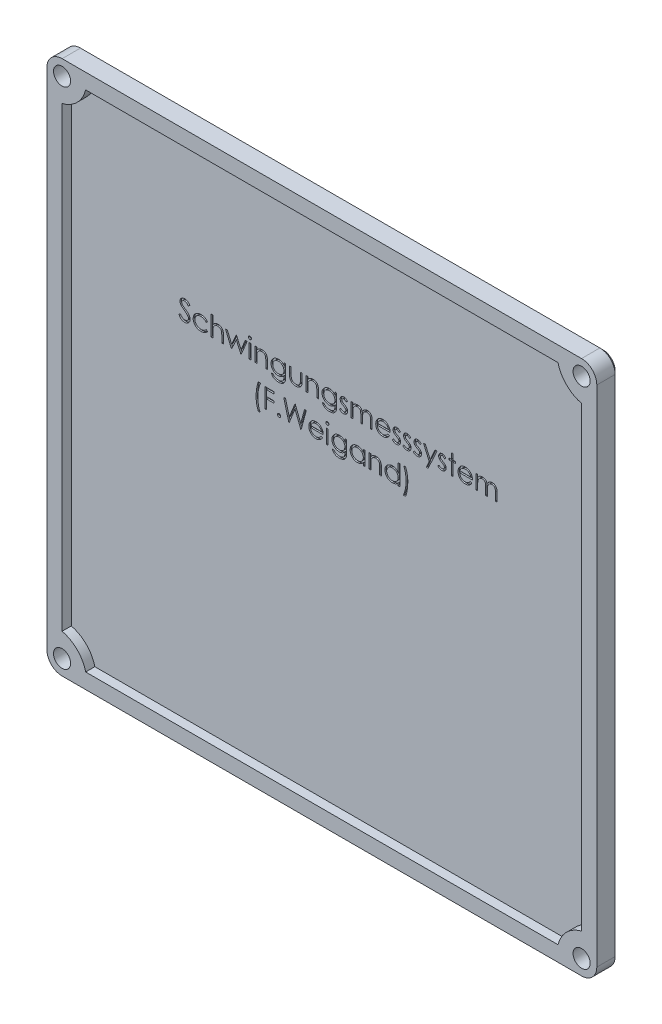
from build123d import *
from build123d.topology import SkipClean

# Parameters (mm, degrees)
SKIZZE1_W                       = 180
SKIZZE1_H                       = 175
SKIZZE1_W_2                     = 170
SKIZZE1_H_2                     = 165
AUFSATZ_LINEAR_AUSTRAGEN1_DEPTH = 3
SKIZZE1_2_W                     = 180
SKIZZE1_2_H                     = 175
AUFSATZ_LINEAR_AUSTRAGEN2_DEPTH = 4
SKIZZE2_R                       = 2.8
SCHNITT_LINEAR_AUSTRAGEN2_DEPTH = 126.718932544
VERRUNDUNG1_R                   = 5
FASE1_SIZE                      = 1
AUFSATZ_LINEAR_AUSTRAGEN3_DEPTH = 3
SKIZZE3_W                       = 0.569871795
SKIZZE3_H                       = 4.640384615
SKIZZE3_W_2                     = 0.569871794
SCHNITT_LINEAR_AUSTRAGEN3_DEPTH = 0.5


with BuildPart() as part:
    # Skizze1 → Aufsatz-Linear austragen1 (new body)
    with BuildSketch(Plane.XY):
        Rectangle(SKIZZE1_W, SKIZZE1_H)
        Rectangle(SKIZZE1_W_2, SKIZZE1_H_2, mode=Mode.SUBTRACT)
    extrude(amount=AUFSATZ_LINEAR_AUSTRAGEN1_DEPTH)

    # Skizze1<2> → Aufsatz-Linear austragen2 (add)
    with BuildSketch(Plane.XY):
        Rectangle(SKIZZE1_2_W, SKIZZE1_2_H)
    extrude(amount=-AUFSATZ_LINEAR_AUSTRAGEN2_DEPTH)

    # Skizze2 → Schnitt-Linear austragen2 (cut, through all)
    with BuildSketch(Plane.XY.offset(3)):
        with Locations((-85.025126266, 82.525126266)):
            Circle(SKIZZE2_R)
        with Locations(Location((85.025126266, 82.525126266, 0), (0, 0, 269.485839889))):
            Circle(SKIZZE2_R)
        with Locations((85.025126266, -82.525126266)):
            Circle(SKIZZE2_R)
        with Locations(Location((-85.025126266, -82.525126266, 0), (0, 0, 0.514160111))):
            Circle(SKIZZE2_R)
    extrude(amount=-SCHNITT_LINEAR_AUSTRAGEN2_DEPTH, mode=Mode.SUBTRACT)

    # Verrundung1
    verrundung1_edges = [part.edges().sort_by_distance(p)[0] for p in [
        (-90, 87.5, -0.5),
        (90, 87.5, -0.5),
        (90, -87.5, -0.5),
        (-90, -87.5, -0.5),
    ]]
    fillet(verrundung1_edges, radius=VERRUNDUNG1_R)

    # Fase1
    fase1_edges = [part.edges().sort_by_distance(p)[0] for p in [
        (0, -87.5, -4),
        (90, 0, -4),
        (-90, 0, -4),
        (0, 87.5, -4),
        (-88.535533906, 86.035533906, -4),
        (88.535533906, 86.035533906, -4),
        (88.535533906, -86.035533906, -4),
        (-88.535533906, -86.035533906, -4),
    ]]
    chamfer(fase1_edges, length=FASE1_SIZE)

    # Skizze2<5> → Aufsatz-Linear austragen3 (add)
    with SkipClean():  # the faces are left unmerged after this step: merging them gives an invalid solid
        with BuildSketch(Plane.XY.offset(3)):
            with BuildLine():
                Line((-87.5, 81.21554618), (-87.5, 74.5))
                ThreePointArc((-87.5, 74.5), (-80.075378798, 77.575378798), (-77, 85))
                Line((-77, 85), (-83.71554618, 85))
                ThreePointArc((-83.71554618, 85), (-83.045227279, 80.545227279), (-87.5, 81.21554618))
            make_face()
            with BuildLine():
                Line((87.5, 74.5), (87.5, 81.21554618))
                ThreePointArc((87.5, 81.21554618), (83.045227279, 80.545227279), (83.71554618, 85))
                Line((83.71554618, 85), (77, 85))
                ThreePointArc((77, 85), (80.075378798, 77.575378798), (87.5, 74.5))
            make_face()
            with BuildLine():
                Line((77, -85), (83.71554618, -85))
                ThreePointArc((83.71554618, -85), (83.045227279, -80.545227279), (87.5, -81.21554618))
                Line((87.5, -81.21554618), (87.5, -74.5))
                ThreePointArc((87.5, -74.5), (80.075378798, -77.575378798), (77, -85))
            make_face()
            with BuildLine():
                Line((-87.5, -74.5), (-87.5, -81.21554618))
                ThreePointArc((-87.5, -81.21554618), (-83.045227279, -80.545227279), (-83.71554618, -85))
                Line((-83.71554618, -85), (-77, -85))
                ThreePointArc((-77, -85), (-80.075378798, -77.575378798), (-87.5, -74.5))
            make_face()
        extrude(amount=-AUFSATZ_LINEAR_AUSTRAGEN3_DEPTH)

    # Skizze3 → Schnitt-Linear austragen3 (cut)
    # profile 1 of 34: a face of its own
    with SkipClean():  # the faces are left unmerged after this step: merging them gives an invalid solid
        with BuildSketch(Plane.XY):
            with BuildLine():
                Line((-49.837179487, 31.224969952), (-49.300380609, 31.546794872))
                add(Edge.make_bspline(
                    [(-49.300380609, 31.546794872), (-49.250454664, 31.463220916), (-49.154798481, 31.303096443), (-48.995229586, 31.086728284), (-48.829888448, 30.902828371), (-48.657550657, 30.752466525), (-48.479268151, 30.634086402), (-48.293877082, 30.550262353), (-48.102002197, 30.497981941), (-47.971421121, 30.491631784), (-47.906229968, 30.488461538)],
                    knots=[0, 0, 0, 0, 1.272034388, 2.437168799, 3.508375237, 4.49857839, 5.41946034, 6.295179144, 7.148887113, 8, 8, 8, 8], degree=3))
                add(Edge.make_bspline(
                    [(-47.906229968, 30.488461538), (-47.850555235, 30.490012159), (-47.740179947, 30.493086267), (-47.577688449, 30.522624293), (-47.419878608, 30.568003441), (-47.270002937, 30.632992846), (-47.130129464, 30.711621241), (-47.007471603, 30.806592163), (-46.901433655, 30.912920565), (-46.814694261, 31.031543381), (-46.748146197, 31.15911878), (-46.69699773, 31.290066577), (-46.668613097, 31.426443837), (-46.664337272, 31.518265676), (-46.662179487, 31.564603365)],
                    knots=[0, 0, 0, 0, 1.095163259, 2.171163733, 3.241058638, 4.321873601, 5.38011039, 6.391990106, 7.366004449, 8.327778327, 9.272591725, 10.192022065, 11.087607919, 12, 12, 12, 12], degree=3))
                add(Edge.make_bspline(
                    [(-46.662179487, 31.564603365), (-46.664854308, 31.617473193), (-46.670291828, 31.724949826), (-46.71625037, 31.883517768), (-46.78854829, 32.040440002), (-46.855246229, 32.137506584), (-46.889873798, 32.187900641)],
                    knots=[0, 0, 0, 0, 0.938893495, 1.908633276, 2.914225137, 4, 4, 4, 4], degree=3))
                add(Edge.make_bspline(
                    [(-46.889873798, 32.187900641), (-46.91830477, 32.224271307), (-46.977992038, 32.30062697), (-47.080603525, 32.414283326), (-47.201010618, 32.5315196), (-47.335092782, 32.65681246), (-47.487734243, 32.784334606), (-47.654154162, 32.920167053), (-47.838601449, 33.0591442), (-47.967959107, 33.152348712), (-48.034705529, 33.200440705)],
                    knots=[0, 0, 0, 0, 0.722233717, 1.516239348, 2.393582979, 3.351407094, 4.387010283, 5.505090956, 6.712668013, 8, 8, 8, 8], degree=3))
                add(Edge.make_bspline(
                    [(-48.034705529, 33.200440705), (-48.101514779, 33.248026857), (-48.229248978, 33.339007956), (-48.407880977, 33.474034871), (-48.567618789, 33.597485891), (-48.707752433, 33.71052317), (-48.828220273, 33.813162039), (-48.929971605, 33.904416871), (-49.010414415, 33.986755618), (-49.055146683, 34.040170623), (-49.075230369, 34.064152644)],
                    knots=[0, 0, 0, 0, 1.452282411, 2.77665338, 3.964542531, 5.026858415, 5.96415736, 6.766646006, 7.446254459, 8, 8, 8, 8], degree=3))
                add(Edge.make_bspline(
                    [(-49.075230369, 34.064152644), (-49.103301986, 34.101528811), (-49.15850859, 34.175034059), (-49.2313812, 34.289923444), (-49.293319395, 34.407531369), (-49.341873912, 34.528173866), (-49.382761052, 34.650157237), (-49.410261869, 34.775073068), (-49.427481975, 34.902360847), (-49.429245436, 34.988019627), (-49.430128205, 35.030899439)],
                    knots=[0, 0, 0, 0, 1.068054152, 2.10047183, 3.106115577, 4.101338837, 5.06977816, 6.043150881, 7.020423561, 8, 8, 8, 8], degree=3))
                add(Edge.make_bspline(
                    [(-49.430128205, 35.030899439), (-49.427760183, 35.09808203), (-49.423074754, 35.231011231), (-49.383449815, 35.425195738), (-49.320906137, 35.610591095), (-49.233285412, 35.785361843), (-49.120332786, 35.944957266), (-48.989620804, 36.091213164), (-48.83393425, 36.214164734), (-48.663114491, 36.321592326), (-48.476140787, 36.405677076), (-48.280214434, 36.469106283), (-48.075024032, 36.505045936), (-47.936044059, 36.510203524), (-47.86552484, 36.512820513)],
                    knots=[0, 0, 0, 0, 1.005424448, 1.989358655, 2.955360095, 3.929531133, 4.905563448, 5.876582895, 6.856512386, 7.866279853, 8.892233794, 9.918561126, 10.94386622, 12, 12, 12, 12], degree=3))
                add(Edge.make_bspline(
                    [(-47.86552484, 36.512820513), (-47.790696258, 36.510239598), (-47.641886091, 36.505106981), (-47.422993943, 36.460480032), (-47.212245214, 36.386637384), (-47.042712434, 36.302837962), (-46.91002871, 36.219142394), (-46.808841037, 36.142906427), (-46.706302234, 36.055140158), (-46.601585192, 35.955609812), (-46.496464281, 35.843402135), (-46.389378875, 35.719285599), (-46.280078558, 35.584018705), (-46.209764355, 35.487454254), (-46.173717949, 35.437950721)],
                    knots=[0, 0, 0, 0, 1.286793592, 2.559021753, 3.825965368, 5.121522368, 5.803751409, 6.523245864, 7.299691795, 8.125521123, 9.008227632, 9.944561021, 10.946284179, 12, 12, 12, 12], degree=3))
                Line((-46.173717949, 35.437950721), (-46.688892228, 35.047435897))
                add(Edge.make_bspline(
                    [(-46.688892228, 35.047435897), (-46.719999848, 35.087511093), (-46.779905851, 35.164686549), (-46.870855063, 35.272765936), (-46.95657761, 35.371492978), (-47.041033336, 35.457245424), (-47.119761781, 35.534719295), (-47.196174129, 35.601049139), (-47.269170738, 35.656884863), (-47.361185704, 35.716472464), (-47.476787851, 35.775539263), (-47.621902652, 35.825521162), (-47.773552037, 35.855556775), (-47.876838654, 35.859528042), (-47.929126603, 35.861538462)],
                    knots=[0, 0, 0, 0, 1.181633172, 2.275549214, 3.290209073, 4.226197932, 5.078386478, 5.862611352, 6.581680152, 7.217281963, 8.414376989, 9.595101626, 10.782541182, 12, 12, 12, 12], degree=3))
                add(Edge.make_bspline(
                    [(-47.929126603, 35.861538462), (-47.994724865, 35.859340092), (-48.121224934, 35.855100742), (-48.300821505, 35.808800198), (-48.46246334, 35.735898822), (-48.601351565, 35.633727362), (-48.716988652, 35.512676418), (-48.800637128, 35.373377638), (-48.850983855, 35.219558137), (-48.857127533, 35.112258274), (-48.86025641, 35.057612179)],
                    knots=[0, 0, 0, 0, 1.14458467, 2.207223713, 3.21896685, 4.227309161, 5.202851033, 6.127160689, 7.046193047, 8, 8, 8, 8], degree=3))
                add(Edge.make_bspline(
                    [(-48.86025641, 35.057612179), (-48.859543166, 35.02359164), (-48.858115512, 34.95549493), (-48.838204093, 34.854890208), (-48.812623882, 34.754539635), (-48.772087964, 34.654894377), (-48.716125771, 34.554211754), (-48.642637809, 34.450758031), (-48.550085085, 34.343621359), (-48.47918822, 34.27393941), (-48.441756811, 34.237149439)],
                    knots=[0, 0, 0, 0, 0.858281714, 1.717966888, 2.583508476, 3.4729293, 4.427298488, 5.488583878, 6.674047936, 8, 8, 8, 8], degree=3))
                add(Edge.make_bspline(
                    [(-48.441756811, 34.237149439), (-48.427856892, 34.224745121), (-48.394833868, 34.1952753), (-48.334461831, 34.147029305), (-48.25473704, 34.087515704), (-48.157741332, 34.013878716), (-48.041686262, 33.928459491), (-47.906559067, 33.832350224), (-47.753866, 33.722430891), (-47.645513381, 33.64558221), (-47.588221154, 33.604947917)],
                    knots=[0, 0, 0, 0, 0.420754252, 0.999615792, 1.744751191, 2.668019286, 3.750313428, 4.999500688, 6.413464383, 8, 8, 8, 8], degree=3))
                add(Edge.make_bspline(
                    [(-47.588221154, 33.604947917), (-47.519303854, 33.554798593), (-47.385855055, 33.457691378), (-47.195976302, 33.311794359), (-47.023811822, 33.169104836), (-46.868757153, 33.030534034), (-46.729280476, 32.897133065), (-46.606929183, 32.76729701), (-46.500456591, 32.641956042), (-46.385831438, 32.481260083), (-46.268705108, 32.283900116), (-46.168118373, 32.042095312), (-46.104693943, 31.799350559), (-46.096399908, 31.636197584), (-46.092307692, 31.555699119)],
                    knots=[0, 0, 0, 0, 1.163667725, 2.253281268, 3.268753668, 4.215851969, 5.092017293, 5.902905408, 6.650798638, 7.335211899, 8.59617414, 9.77448103, 10.901945474, 12, 12, 12, 12], degree=3))
                add(Edge.make_bspline(
                    [(-46.092307692, 31.555699119), (-46.093499929, 31.498769799), (-46.095861249, 31.386016689), (-46.123004621, 31.220453907), (-46.162773156, 31.059652186), (-46.222712138, 30.905599168), (-46.295869868, 30.755476527), (-46.38870006, 30.613222193), (-46.496301146, 30.475687727), (-46.619733833, 30.346540536), (-46.75479997, 30.227983866), (-46.897554674, 30.12252114), (-47.048231597, 30.034585753), (-47.206013343, 29.962829226), (-47.370936154, 29.906706987), (-47.542944562, 29.866043638), (-47.722322104, 29.841086848), (-47.844242978, 29.838496481), (-47.906229968, 29.837179487)],
                    knots=[0, 0, 0, 0, 0.983748083, 1.948392443, 2.894712957, 3.844097841, 4.80183111, 5.778335162, 6.776009319, 7.81870978, 8.863265674, 9.881300176, 10.883814829, 11.87499822, 12.874611388, 13.892143829, 14.928324115, 16, 16, 16, 16], degree=3))
                add(Edge.make_bspline(
                    [(-47.906229968, 29.837179487), (-47.954191233, 29.838106917), (-48.049509741, 29.839950096), (-48.190496943, 29.856244704), (-48.328635912, 29.879299021), (-48.462193253, 29.915900548), (-48.592889699, 29.960308778), (-48.720156825, 30.014988324), (-48.844056308, 30.080515246), (-48.965282494, 30.15543622), (-49.083527068, 30.242626699), (-49.19768096, 30.344178614), (-49.311489625, 30.457291173), (-49.421593902, 30.585036052), (-49.530220892, 30.725349431), (-49.635228863, 30.879544093), (-49.738791408, 31.046780149), (-49.8037709, 31.164463947), (-49.837179487, 31.224969952)],
                    knots=[0, 0, 0, 0, 0.915332311, 1.819136955, 2.706846663, 3.586547465, 4.459518054, 5.340707479, 6.227863349, 7.133153174, 8.059268498, 9.028702269, 10.047606654, 11.120612155, 12.245963614, 13.433783089, 14.680604001, 16, 16, 16, 16], degree=3))
            make_face()
        # profile 2 of 34: a face of its own
        with BuildSketch(Plane.XY):
            with BuildLine():
                Line((-40.393589744, 33.634204728), (-40.870602965, 33.337820513))
                add(Edge.make_bspline(
                    [(-40.870602965, 33.337820513), (-40.922908578, 33.402823456), (-41.025863296, 33.530770713), (-41.204641625, 33.695888735), (-41.395162334, 33.837706082), (-41.600681077, 33.953282887), (-41.8209096, 34.042584662), (-42.054979402, 34.105776606), (-42.302857104, 34.145154304), (-42.472792536, 34.149629851), (-42.559865785, 34.151923077)],
                    knots=[0, 0, 0, 0, 1.026593902, 2.0206758, 2.988051866, 3.946915611, 4.916868779, 5.907761954, 6.927957743, 8, 8, 8, 8], degree=3))
                add(Edge.make_bspline(
                    [(-42.559865785, 34.151923077), (-42.629459893, 34.150005663), (-42.766523595, 34.146229369), (-42.967739045, 34.122624617), (-43.159404457, 34.079731259), (-43.342721172, 34.023214523), (-43.51638536, 33.947467569), (-43.680852026, 33.855284154), (-43.837579987, 33.748150509), (-43.982027503, 33.624034234), (-44.11416013, 33.489053794), (-44.228639589, 33.344357804), (-44.328310882, 33.194280287), (-44.406517402, 33.035073555), (-44.47051664, 32.870379858), (-44.512620261, 32.697090434), (-44.540677637, 32.517425335), (-44.543887705, 32.394927776), (-44.545512821, 32.33291266)],
                    knots=[0, 0, 0, 0, 1.112346261, 2.190735716, 3.231507886, 4.247384806, 5.251966152, 6.253067467, 7.256802811, 8.280671706, 9.291813951, 10.270744147, 11.225547591, 12.165006084, 13.100104208, 14.043489273, 15.009504848, 16, 16, 16, 16], degree=3))
                add(Edge.make_bspline(
                    [(-44.545512821, 32.33291266), (-44.542284749, 32.25168852), (-44.5358721, 32.090334665), (-44.485613738, 31.85215868), (-44.403346027, 31.621882842), (-44.290755355, 31.401142079), (-44.148375412, 31.196864112), (-43.981148047, 31.013651273), (-43.788980567, 30.855053622), (-43.573566196, 30.723567755), (-43.339962861, 30.617864988), (-43.090697957, 30.542558827), (-42.827808355, 30.497106665), (-42.647818971, 30.491380883), (-42.556049679, 30.488461538)],
                    knots=[0, 0, 0, 0, 0.966302908, 1.919585723, 2.883856336, 3.870342332, 4.860282998, 5.839159637, 6.814385684, 7.815993281, 8.834850808, 9.858348828, 10.908058873, 12, 12, 12, 12], degree=3))
                add(Edge.make_bspline(
                    [(-42.556049679, 30.488461538), (-42.471948131, 30.490819198), (-42.30666627, 30.495452624), (-42.065062767, 30.534512314), (-41.835047786, 30.598454335), (-41.616629501, 30.687622215), (-41.410207029, 30.802879279), (-41.217114097, 30.945045203), (-41.033508495, 31.110030178), (-40.92556398, 31.237607069), (-40.870602965, 31.302564103)],
                    knots=[0, 0, 0, 0, 1.039848629, 2.043578496, 3.018386758, 3.987534228, 4.954977003, 5.934852016, 6.948509513, 8, 8, 8, 8], degree=3))
                Line((-40.870602965, 31.302564103), (-40.393589744, 30.989643429))
                add(Edge.make_bspline(
                    [(-40.393589744, 30.989643429), (-40.421870289, 30.948113111), (-40.478337513, 30.865190317), (-40.572730491, 30.748270277), (-40.6745479, 30.638829511), (-40.783392518, 30.537014717), (-40.897843122, 30.440389454), (-41.021809472, 30.353573026), (-41.151294339, 30.271685562), (-41.287817811, 30.198002208), (-41.429968363, 30.13176931), (-41.577545972, 30.074816757), (-41.729909347, 30.02588528), (-41.887237629, 29.986991808), (-42.049840988, 29.955947858), (-42.217298896, 29.935348999), (-42.38955368, 29.919972418), (-42.505980297, 29.919054631), (-42.564953926, 29.918589744)],
                    knots=[0, 0, 0, 0, 0.954134338, 1.905101784, 2.851144739, 3.791306361, 4.734911809, 5.6936923, 6.663572882, 7.643865596, 8.638447847, 9.640600242, 10.646758161, 11.676244097, 12.717260333, 13.78922464, 14.880174919, 16, 16, 16, 16], degree=3))
                add(Edge.make_bspline(
                    [(-42.564953926, 29.918589744), (-42.654962244, 29.92020678), (-42.831379199, 29.923376183), (-43.089592892, 29.958225845), (-43.336360545, 30.010763235), (-43.571597852, 30.086171723), (-43.795341434, 30.183244673), (-44.007382663, 30.301820789), (-44.207019439, 30.442884751), (-44.392277573, 30.603925775), (-44.562423911, 30.778533795), (-44.708521428, 30.966947218), (-44.835240705, 31.162238833), (-44.936999533, 31.36872183), (-45.018001814, 31.583651863), (-45.073346296, 31.808750727), (-45.109141677, 32.042162674), (-45.11328438, 32.201335189), (-45.115384615, 32.28203125)],
                    knots=[0, 0, 0, 0, 1.1129367, 2.181364009, 3.217532258, 4.231199276, 5.232079859, 6.230262199, 7.231623845, 8.250719726, 9.263571943, 10.242672461, 11.195837495, 12.138959767, 13.085126421, 14.0317438, 15.002148558, 16, 16, 16, 16], degree=3))
                add(Edge.make_bspline(
                    [(-45.115384615, 32.28203125), (-45.114584486, 32.336783553), (-45.112992897, 32.44569492), (-45.094737685, 32.607338826), (-45.071154741, 32.766830044), (-45.031193761, 32.922146907), (-44.985037187, 33.075645076), (-44.926117293, 33.225474417), (-44.857001363, 33.37233118), (-44.778529972, 33.515837061), (-44.690194678, 33.653631226), (-44.592438726, 33.783812874), (-44.488944002, 33.907945877), (-44.37486877, 34.0217447), (-44.255053969, 34.129760362), (-44.126109825, 34.229107244), (-43.988775923, 34.320077328), (-43.845114752, 34.404352742), (-43.695209918, 34.479390574), (-43.539967531, 34.544039448), (-43.380323035, 34.599289122), (-43.216021059, 34.64302959), (-43.048152145, 34.679709772), (-42.875393431, 34.702783579), (-42.698405828, 34.719087245), (-42.57856133, 34.720884825), (-42.517888622, 34.721794872)],
                    knots=[0, 0, 0, 0, 0.990994727, 1.971252077, 2.943264845, 3.907940874, 4.872158414, 5.844625996, 6.82015047, 7.809835459, 8.804511986, 9.781214284, 10.756496977, 11.728388426, 12.696359165, 13.676225489, 14.672885716, 15.677705647, 16.690706858, 17.706033469, 18.721040654, 19.747369689, 20.783475414, 21.830280724, 22.901553713, 24, 24, 24, 24], degree=3))
                add(Edge.make_bspline(
                    [(-42.517888622, 34.721794872), (-42.44190614, 34.720122298), (-42.290320973, 34.716785511), (-42.065457119, 34.688702813), (-41.843905267, 34.646363886), (-41.629552665, 34.583638895), (-41.424998275, 34.507686263), (-41.233526815, 34.422391766), (-41.059645484, 34.323341557), (-40.900119715, 34.214992207), (-40.754651162, 34.092780278), (-40.621746583, 33.955244798), (-40.498680591, 33.803101558), (-40.428909128, 33.690968302), (-40.393589744, 33.634204728)],
                    knots=[0, 0, 0, 0, 1.095225653, 2.184976855, 3.262915854, 4.344593502, 5.400796181, 6.407717688, 7.363229445, 8.282371371, 9.184954523, 10.097238608, 11.036792983, 12, 12, 12, 12], degree=3))
            make_face()
        # profile 3 of 34: a face of its own
        with BuildSketch(Plane.XY):
            with BuildLine():
                Line((-39.253846154, 36.512820513), (-38.683974359, 36.512820513))
                Line((-38.683974359, 36.512820513), (-38.683974359, 33.763952324))
                add(Edge.make_bspline(
                    [(-38.683974359, 33.763952324), (-38.62280154, 33.840413548), (-38.503694928, 33.989287471), (-38.303223402, 34.18352706), (-38.09735482, 34.351890273), (-37.878978665, 34.485912388), (-37.652101292, 34.591787831), (-37.415765823, 34.666876846), (-37.169928346, 34.713052408), (-37.002968431, 34.718855251), (-36.918389423, 34.721794872)],
                    knots=[0, 0, 0, 0, 1.125788106, 2.19196713, 3.20547328, 4.180437432, 5.132270164, 6.079753143, 7.027236121, 8, 8, 8, 8], degree=3))
                add(Edge.make_bspline(
                    [(-36.918389423, 34.721794872), (-36.832518568, 34.718628163), (-36.66444859, 34.712430149), (-36.419735079, 34.663420158), (-36.191206063, 34.579677377), (-35.979540891, 34.465074346), (-35.789358941, 34.322339359), (-35.62090294, 34.157545025), (-35.483306062, 33.96654806), (-35.389690521, 33.790097427), (-35.328778767, 33.633091402), (-35.290221882, 33.498405159), (-35.257529908, 33.348323973), (-35.229046102, 33.182925102), (-35.210062175, 33.001414577), (-35.194813797, 32.804611286), (-35.183970801, 32.592526515), (-35.183550605, 32.445714062), (-35.183333333, 32.369801683)],
                    knots=[0, 0, 0, 0, 1.235656852, 2.418478516, 3.575258207, 4.727955599, 5.870717718, 6.98870536, 8.107142894, 9.245821548, 9.854588956, 10.528768408, 11.260415777, 12.065282286, 12.943670737, 13.886611085, 14.907229059, 16, 16, 16, 16], degree=3))
                Line((-35.183333333, 32.369801683), (-35.183333333, 30))
                Line((-35.183333333, 30), (-35.753205128, 30))
                Line((-35.753205128, 30), (-35.753205128, 32.1828125))
                add(Edge.make_bspline(
                    [(-35.753205128, 32.1828125), (-35.753550393, 32.245990772), (-35.754210824, 32.366840054), (-35.756394035, 32.539861422), (-35.761267597, 32.696790123), (-35.769143096, 32.837123221), (-35.777425868, 32.961056359), (-35.7888256, 33.068409557), (-35.802088453, 33.159330264), (-35.8140061, 33.214057519), (-35.819350962, 33.238601763)],
                    knots=[0, 0, 0, 0, 1.430932559, 2.737130458, 3.918967929, 4.986496826, 5.920444988, 6.731744033, 7.431208747, 8, 8, 8, 8], degree=3))
                add(Edge.make_bspline(
                    [(-35.819350962, 33.238601763), (-35.840077806, 33.310618498), (-35.879925044, 33.449070253), (-35.97254066, 33.637143483), (-36.088217723, 33.797498655), (-36.229454898, 33.927971721), (-36.393753644, 34.030318371), (-36.582185293, 34.10119849), (-36.792976389, 34.145190785), (-36.941478345, 34.149616379), (-37.018880208, 34.151923077)],
                    knots=[0, 0, 0, 0, 1.090059168, 2.095632401, 3.037101401, 3.955032261, 4.878929692, 5.839099886, 6.873700383, 8, 8, 8, 8], degree=3))
                add(Edge.make_bspline(
                    [(-37.018880208, 34.151923077), (-37.064723168, 34.151059792), (-37.155445201, 34.149351374), (-37.289972067, 34.1321993), (-37.420471939, 34.104170911), (-37.548201604, 34.066244105), (-37.670453977, 34.014635775), (-37.79079251, 33.954891003), (-37.905807718, 33.881760311), (-38.017541985, 33.799707848), (-38.121532367, 33.708866998), (-38.218282991, 33.612987522), (-38.304531122, 33.510888659), (-38.382669852, 33.404208448), (-38.450121884, 33.291483623), (-38.509001048, 33.173801216), (-38.558958668, 33.051006467), (-38.583782981, 32.965780283), (-38.596203926, 32.923137019)],
                    knots=[0, 0, 0, 0, 1.024319606, 2.027102035, 3.025350316, 4.005802111, 5.00026367, 5.987881639, 7.005602596, 8.042517216, 9.083927026, 10.089214625, 11.084353441, 12.06828073, 13.041928858, 14.016821737, 15.00770877, 16, 16, 16, 16], degree=3))
                add(Edge.make_bspline(
                    [(-38.596203926, 32.923137019), (-38.603351173, 32.892256151), (-38.618925903, 32.824962939), (-38.635825672, 32.713975237), (-38.650952817, 32.585004247), (-38.6637409, 32.438245587), (-38.671584214, 32.273161476), (-38.680035594, 32.09087845), (-38.683181591, 31.890254698), (-38.683702205, 31.750744278), (-38.683974359, 31.677814503)],
                    knots=[0, 0, 0, 0, 0.607992626, 1.324890765, 2.152360218, 3.099583803, 4.150613268, 5.323148443, 6.60066238, 8, 8, 8, 8], degree=3))
                Line((-38.683974359, 31.677814503), (-38.683974359, 30))
                Line((-38.683974359, 30), (-39.253846154, 30))
                Line((-39.253846154, 30), (-39.253846154, 36.512820513))
            make_face()
        # profile 4 of 34: a face of its own
        with BuildSketch(Plane.XY):
            Polygon((-34.532051282, 34.640384615), (-33.920202324, 34.640384615), (-32.5375, 31.302564103), (-31.02250601, 34.640384615), (-30.92583133, 34.640384615), (-29.443910256, 31.302564103), (-28.04848758, 34.640384615), (-27.449358974, 34.640384615), (-29.38921274, 30), (-29.507512019, 30), (-30.990705128, 33.337820513), (-32.504427083, 30), (-32.61000601, 30), align=None)
        # profile 5 of 34: a face of its own
        with BuildSketch(Plane.XY):
            with BuildLine():
                add(Edge.make_bspline(
                    [(-26.515685096, 36.594230769), (-26.48032228, 36.592590378), (-26.411075095, 36.589378178), (-26.310938738, 36.561870927), (-26.219758159, 36.515244355), (-26.138881415, 36.452688362), (-26.069481564, 36.379120086), (-26.020893703, 36.293375187), (-25.989665499, 36.200740228), (-25.985894406, 36.13612428), (-25.983974359, 36.10322516)],
                    knots=[0, 0, 0, 0, 1.055194115, 2.066272739, 3.074728998, 4.095836921, 5.109056067, 6.073838105, 7.019297344, 8, 8, 8, 8], degree=3))
                add(Edge.make_bspline(
                    [(-25.983974359, 36.10322516), (-25.985937706, 36.071180061), (-25.989819011, 36.007830692), (-26.020869583, 35.916801678), (-26.069895643, 35.832248193), (-26.138836913, 35.758822761), (-26.219769951, 35.696301351), (-26.310935606, 35.64966561), (-26.411075919, 35.622160789), (-26.480322559, 35.618948254), (-26.515685096, 35.617307692)],
                    knots=[0, 0, 0, 0, 0.96129708, 1.900370562, 2.859976407, 3.87933698, 4.906634145, 5.921202961, 6.938410037, 8, 8, 8, 8], degree=3))
                add(Edge.make_bspline(
                    [(-26.515685096, 35.617307692), (-26.550643253, 35.618885613), (-26.618684737, 35.62195683), (-26.717321722, 35.650205291), (-26.807724838, 35.696317309), (-26.888759316, 35.758413388), (-26.956305523, 35.83269913), (-27.005469628, 35.916750078), (-27.036448488, 36.00784383), (-27.040339457, 36.071184474), (-27.042307692, 36.10322516)],
                    knots=[0, 0, 0, 0, 1.054934014, 2.053291228, 3.073705704, 4.106921865, 5.123545215, 6.088680038, 7.033164197, 8, 8, 8, 8], degree=3))
                add(Edge.make_bspline(
                    [(-27.042307692, 36.10322516), (-27.040382578, 36.136119702), (-27.036601532, 36.200726657), (-27.005446407, 36.293427645), (-26.956715042, 36.378665512), (-26.888714591, 36.45309749), (-26.807736741, 36.515228493), (-26.717318646, 36.561331274), (-26.618685549, 36.589582132), (-26.550643528, 36.592653018), (-26.515685096, 36.594230769)],
                    knots=[0, 0, 0, 0, 0.98631895, 1.937192651, 2.907499808, 3.917963147, 4.944918757, 5.95915025, 6.951458133, 8, 8, 8, 8], degree=3))
            make_face()
        # profile 6 of 34: a face of its own
        with BuildSketch(Plane.XY):
            with Locations((-26.513141026, 32.320192308)):
                Rectangle(SKIZZE3_W, SKIZZE3_H)
        # profile 7 of 34: a face of its own
        with BuildSketch(Plane.XY):
            with BuildLine():
                Line((-24.844230769, 34.640384615), (-24.274358974, 34.640384615))
                Line((-24.274358974, 34.640384615), (-24.274358974, 33.803385417))
                add(Edge.make_bspline(
                    [(-24.274358974, 33.803385417), (-24.213512122, 33.879300071), (-24.095436682, 34.026615106), (-23.898796535, 34.22023672), (-23.690981173, 34.379794485), (-23.473263252, 34.506982797), (-23.24534722, 34.602861676), (-23.008622358, 34.67210558), (-22.761671392, 34.713625197), (-22.593733056, 34.719050329), (-22.508774038, 34.721794872)],
                    knots=[0, 0, 0, 0, 1.12780773, 2.188550248, 3.19190651, 4.159438251, 5.104880172, 6.052711206, 7.014878035, 8, 8, 8, 8], degree=3))
                add(Edge.make_bspline(
                    [(-22.508774038, 34.721794872), (-22.422902745, 34.718628589), (-22.254831911, 34.712431409), (-22.010124571, 34.663415412), (-21.781572842, 34.579694735), (-21.569991648, 34.465009979), (-21.379260847, 34.322395377), (-21.211757188, 34.156247116), (-21.073212439, 33.965137365), (-20.980325795, 33.787839638), (-20.919137834, 33.630561397), (-20.880616307, 33.495856579), (-20.847902955, 33.345782219), (-20.819542498, 33.180791822), (-20.800352595, 32.999729391), (-20.785217295, 32.80333715), (-20.774370235, 32.591678713), (-20.773939874, 32.445290118), (-20.773717949, 32.369801683)],
                    knots=[0, 0, 0, 0, 1.235846778, 2.418850247, 3.575807741, 4.728682307, 5.871620074, 6.994088408, 8.11269785, 9.256955736, 9.865816715, 10.540099792, 11.271859618, 12.076849838, 12.949306005, 13.892391288, 14.913166135, 16, 16, 16, 16], degree=3))
                Line((-20.773717949, 32.369801683), (-20.773717949, 30))
                Line((-20.773717949, 30), (-21.343589744, 30))
                Line((-21.343589744, 30), (-21.343589744, 32.1828125))
                add(Edge.make_bspline(
                    [(-21.343589744, 32.1828125), (-21.343940278, 32.245990364), (-21.344610791, 32.366838867), (-21.346725607, 32.539865523), (-21.351823399, 32.696776887), (-21.358986767, 32.837197825), (-21.369471579, 32.9609935), (-21.380398353, 33.068416045), (-21.393760526, 33.159329072), (-21.405667525, 33.21405715), (-21.411007612, 33.238601763)],
                    knots=[0, 0, 0, 0, 1.430800155, 2.736877192, 3.918605307, 4.986035426, 5.920637409, 6.731861385, 7.431261377, 8, 8, 8, 8], degree=3))
                add(Edge.make_bspline(
                    [(-21.411007612, 33.238601763), (-21.430285362, 33.310649198), (-21.467389067, 33.449318221), (-21.55907215, 33.637413118), (-21.674849307, 33.79742983), (-21.816178262, 33.928379025), (-21.981693871, 34.030288971), (-22.17093683, 34.100998861), (-22.382080935, 34.145224378), (-22.530588172, 34.149627889), (-22.607992788, 34.151923077)],
                    knots=[0, 0, 0, 0, 1.084156227, 2.086665306, 3.027808233, 3.945421172, 4.874247719, 5.839848303, 6.874090471, 8, 8, 8, 8], degree=3))
                add(Edge.make_bspline(
                    [(-22.607992788, 34.151923077), (-22.653835586, 34.151059468), (-22.744557297, 34.14935041), (-22.879086532, 34.132203055), (-23.009577532, 34.104156999), (-23.137339911, 34.066295329), (-23.259818337, 34.014293783), (-23.380947837, 33.955276211), (-23.496167252, 33.88171017), (-23.607933415, 33.799721471), (-23.711915223, 33.70886348), (-23.808668066, 33.612988441), (-23.894915617, 33.510888417), (-23.973054499, 33.404208512), (-24.040506491, 33.291483606), (-24.099385665, 33.173801221), (-24.149343283, 33.051006465), (-24.174167596, 32.965780283), (-24.186588542, 32.923137019)],
                    knots=[0, 0, 0, 0, 1.023777757, 2.026029729, 3.023749952, 4.003683103, 4.997618607, 5.993177895, 7.010360494, 8.046726602, 9.087585522, 10.09234134, 11.086953743, 12.070360549, 13.043493632, 14.017870808, 15.008233677, 16, 16, 16, 16], degree=3))
                add(Edge.make_bspline(
                    [(-24.186588542, 32.923137019), (-24.19373619, 32.891831151), (-24.209296246, 32.823679913), (-24.226102301, 32.711839324), (-24.241356045, 32.582462655), (-24.254123098, 32.435700879), (-24.261934354, 32.271040163), (-24.270451331, 32.089183715), (-24.273552056, 31.889406386), (-24.27408247, 31.750320172), (-24.274358974, 31.677814503)],
                    knots=[0, 0, 0, 0, 0.615963638, 1.340920617, 2.168419149, 3.115676021, 4.16674242, 5.331190069, 6.6087489, 8, 8, 8, 8], degree=3))
                Line((-24.274358974, 31.677814503), (-24.274358974, 30))
                Line((-24.274358974, 30), (-24.844230769, 30))
                Line((-24.844230769, 30), (-24.844230769, 34.640384615))
            make_face()
        # profile 8 of 34: a face of its own
        with BuildSketch(Plane.XY):
            with BuildLine():
                Line((-15.400641026, 34.640384615), (-14.830769231, 34.640384615))
                Line((-14.830769231, 34.640384615), (-14.830769231, 30.957842548))
                add(Edge.make_bspline(
                    [(-14.830769231, 30.957842548), (-14.831271865, 30.879397198), (-14.832242071, 30.727978776), (-14.839228833, 30.509033897), (-14.853962061, 30.306802571), (-14.87066924, 30.120362473), (-14.894702569, 29.950577787), (-14.924051121, 29.796941888), (-14.957135853, 29.659307339), (-14.986201104, 29.574535127), (-14.99994992, 29.534435096)],
                    knots=[0, 0, 0, 0, 1.307562039, 2.523909702, 3.650326591, 4.686913197, 5.643429486, 6.506965704, 7.293745905, 8, 8, 8, 8], degree=3))
                add(Edge.make_bspline(
                    [(-14.99994992, 29.534435096), (-15.020250396, 29.48231081), (-15.060244377, 29.37962072), (-15.135148312, 29.234052738), (-15.219029823, 29.096990002), (-15.314836356, 28.96919634), (-15.422134672, 28.851313285), (-15.538396807, 28.740779743), (-15.665887012, 28.639934183), (-15.80453239, 28.550516571), (-15.951136896, 28.469985773), (-16.105616252, 28.400232716), (-16.267099362, 28.339478014), (-16.43710318, 28.293970656), (-16.612962319, 28.254537663), (-16.796744801, 28.228875161), (-16.987376876, 28.211408927), (-17.116999208, 28.20979379), (-17.18276242, 28.208974359)],
                    knots=[0, 0, 0, 0, 0.981931301, 1.934503488, 2.87077864, 3.801706999, 4.735015492, 5.667491629, 6.616593066, 7.585388521, 8.561939025, 9.551802639, 10.560317337, 11.588439944, 12.640189604, 13.723962949, 14.845264515, 16, 16, 16, 16], degree=3))
                add(Edge.make_bspline(
                    [(-17.18276242, 28.208974359), (-17.278710438, 28.210528269), (-17.466122697, 28.213563473), (-17.739363184, 28.248925561), (-17.998869033, 28.298917067), (-18.241211261, 28.374582628), (-18.464858437, 28.46717831), (-18.668283183, 28.573486296), (-18.849659335, 28.695386899), (-19.013169427, 28.834180846), (-19.160746312, 28.999214954), (-19.299588681, 29.193704286), (-19.433230676, 29.420611356), (-19.511550919, 29.587149565), (-19.552564103, 29.674358974)],
                    knots=[0, 0, 0, 0, 1.157897085, 2.2616841, 3.32207898, 4.345638746, 5.321241055, 6.241986252, 7.112515963, 7.955008012, 8.825025602, 9.77857164, 10.836726669, 12, 12, 12, 12], degree=3))
                Line((-19.552564103, 29.674358974), (-18.982692308, 29.674358974))
                add(Edge.make_bspline(
                    [(-18.982692308, 29.674358974), (-18.936859442, 29.601595457), (-18.847261834, 29.45935174), (-18.679715304, 29.275177872), (-18.496098112, 29.117782481), (-18.290213544, 28.990944363), (-18.061204939, 28.895313741), (-17.808934523, 28.827141418), (-17.531349495, 28.786326762), (-17.33809502, 28.7814077), (-17.237459936, 28.778846154)],
                    knots=[0, 0, 0, 0, 0.997731894, 1.950442991, 2.880492273, 3.800895997, 4.748200782, 5.754801363, 6.83083817, 8, 8, 8, 8], degree=3))
                add(Edge.make_bspline(
                    [(-17.237459936, 28.778846154), (-17.138097149, 28.781440852), (-16.946535642, 28.786443171), (-16.671070521, 28.827159633), (-16.419619705, 28.895328577), (-16.193631912, 28.990775221), (-15.995773589, 29.107706673), (-15.825208977, 29.238335379), (-15.687060778, 29.385620913), (-15.594145825, 29.521296476), (-15.536388733, 29.642171682), (-15.499609103, 29.746225678), (-15.469720616, 29.863887327), (-15.444720053, 29.994762163), (-15.424089968, 30.139037169), (-15.411021881, 30.29704223), (-15.401577052, 30.468418247), (-15.400960249, 30.587241512), (-15.400641026, 30.648737981)],
                    knots=[0, 0, 0, 0, 1.570740765, 3.028230971, 4.391408896, 5.680370741, 6.894727393, 8.017376726, 9.065722033, 10.075533815, 10.603371122, 11.180248986, 11.817768598, 12.521299649, 13.286540596, 14.121245857, 15.027658897, 16, 16, 16, 16], degree=3))
                Line((-15.400641026, 30.648737981), (-15.400641026, 30.889152644))
                add(Edge.make_bspline(
                    [(-15.400641026, 30.889152644), (-15.458482481, 30.820315375), (-15.57314798, 30.683851662), (-15.771172416, 30.505032692), (-15.987465963, 30.351024999), (-16.22166039, 30.224716905), (-16.468019058, 30.123694892), (-16.723873676, 30.053041234), (-16.98693069, 30.007393987), (-17.165188162, 30.002482142), (-17.255268429, 30)],
                    knots=[0, 0, 0, 0, 1.012485704, 2.007162095, 2.997754123, 3.998611389, 4.999708251, 5.992315798, 6.98544096, 8, 8, 8, 8], degree=3))
                add(Edge.make_bspline(
                    [(-17.255268429, 30), (-17.308311375, 30.000934405), (-17.413769558, 30.002792158), (-17.570441743, 30.01904594), (-17.724801967, 30.042629372), (-17.876490229, 30.077248554), (-18.025725413, 30.121683544), (-18.172260901, 30.177231056), (-18.317283156, 30.24003277), (-18.458156088, 30.314006285), (-18.59347664, 30.39630647), (-18.722224133, 30.485458458), (-18.843724197, 30.580995638), (-18.956820399, 30.683860086), (-19.061364388, 30.793902924), (-19.158762263, 30.909951084), (-19.24740345, 31.033625029), (-19.329106885, 31.162669652), (-19.399968441, 31.297944471), (-19.462170087, 31.436516159), (-19.516252864, 31.578088419), (-19.559370093, 31.723135232), (-19.592301399, 31.871565156), (-19.616812811, 32.023135028), (-19.630715558, 32.178311588), (-19.632883492, 32.282853179), (-19.633974359, 32.335456731)],
                    knots=[0, 0, 0, 0, 1.028754217, 2.045334182, 3.052854819, 4.056607503, 5.061168794, 6.071104265, 7.095078842, 8.125279047, 9.155117945, 10.165957491, 11.161587969, 12.151493252, 13.128948131, 14.104219989, 15.088194871, 16.07871515, 17.064853787, 18.047899887, 19.02414258, 20.002704429, 20.980574569, 21.971845993, 22.979467364, 24, 24, 24, 24], degree=3))
                add(Edge.make_bspline(
                    [(-19.633974359, 32.335456731), (-19.633032443, 32.388076634), (-19.631152259, 32.493112634), (-19.614912625, 32.648922377), (-19.591747482, 32.80264578), (-19.555084815, 32.952698352), (-19.51095681, 33.100788973), (-19.456304043, 33.245823801), (-19.390592865, 33.38784701), (-19.316189462, 33.526963775), (-19.232579751, 33.661307304), (-19.140899393, 33.788899933), (-19.041037707, 33.90880276), (-18.934372374, 34.022225411), (-18.819600992, 34.128073548), (-18.696782934, 34.22609027), (-18.567128852, 34.317918575), (-18.430236912, 34.401577716), (-18.288219365, 34.475568363), (-18.144684295, 34.543082646), (-17.997730354, 34.596665977), (-17.850097319, 34.643879314), (-17.699185188, 34.677326025), (-17.546844345, 34.703129235), (-17.392553246, 34.718849515), (-17.289224422, 34.720811819), (-17.237459936, 34.721794872)],
                    knots=[0, 0, 0, 0, 1.008818848, 2.013730394, 3.001654427, 3.987803273, 4.973046549, 5.963777569, 6.957074694, 7.972068341, 8.987420212, 9.989399531, 10.982630087, 11.977756091, 12.973280677, 13.973972381, 14.989194003, 16.018387222, 17.047741039, 18.059210846, 19.057554164, 20.045176975, 21.029480261, 22.018708529, 23.007435371, 24, 24, 24, 24], degree=3))
                add(Edge.make_bspline(
                    [(-17.237459936, 34.721794872), (-17.152096089, 34.719333479), (-16.983528722, 34.714472984), (-16.735459618, 34.67633462), (-16.496078697, 34.615530625), (-16.264035154, 34.528416552), (-16.037438759, 34.409490054), (-15.817036327, 34.252839277), (-15.602190183, 34.057059089), (-15.469606119, 33.906921749), (-15.400641026, 33.828826122)],
                    knots=[0, 0, 0, 0, 0.96728863, 1.910097829, 2.838038873, 3.762875196, 4.71315279, 5.730631239, 6.819562287, 8, 8, 8, 8], degree=3))
                Line((-15.400641026, 33.828826122), (-15.400641026, 34.640384615))
            make_face()
            with BuildLine():
                add(Edge.make_bspline(
                    [(-17.191666667, 34.151923077), (-17.274998087, 34.149090858), (-17.439976628, 34.143483665), (-17.681799764, 34.095614257), (-17.915256486, 34.020600981), (-18.135883477, 33.913299379), (-18.342543519, 33.782499833), (-18.525922122, 33.624039597), (-18.686313898, 33.443071497), (-18.821991515, 33.241231763), (-18.929998423, 33.023477063), (-19.006458627, 32.793950446), (-19.055897955, 32.556360673), (-19.061354695, 32.394213236), (-19.064102564, 32.312560096)],
                    knots=[0, 0, 0, 0, 1.026226791, 2.031711442, 3.026614839, 4.04107745, 5.047145931, 6.032893242, 7.017642609, 8.019221815, 9.021877557, 10.003543541, 10.994637589, 12, 12, 12, 12], degree=3))
                add(Edge.make_bspline(
                    [(-19.064102564, 32.312560096), (-19.062785834, 32.250995445), (-19.06019621, 32.129915778), (-19.035297719, 31.952228455), (-18.995055111, 31.782991314), (-18.938019037, 31.622194121), (-18.867347719, 31.468914564), (-18.77846156, 31.324208524), (-18.673866226, 31.187947129), (-18.554380384, 31.061138206), (-18.422706091, 30.945639021), (-18.279886973, 30.844151433), (-18.126116734, 30.761146553), (-17.965177235, 30.689408176), (-17.793163435, 30.637013296), (-17.612552951, 30.597028654), (-17.422068016, 30.574152765), (-17.292216431, 30.571317404), (-17.226011619, 30.569871795)],
                    knots=[0, 0, 0, 0, 1.039728707, 2.044842319, 3.024901384, 3.974314358, 4.923051295, 5.871625912, 6.837440708, 7.820715446, 8.810779094, 9.792721783, 10.773906224, 11.758876063, 12.764959493, 13.806266761, 14.881525401, 16, 16, 16, 16], degree=3))
                add(Edge.make_bspline(
                    [(-17.226011619, 30.569871795), (-17.1589488, 30.571264457), (-17.027808169, 30.573987793), (-16.836272328, 30.597398426), (-16.654784356, 30.63517544), (-16.483510664, 30.688811215), (-16.321804574, 30.757249248), (-16.17148263, 30.843857111), (-16.029321646, 30.942489724), (-15.899860731, 31.057537235), (-15.782795459, 31.184328583), (-15.680776782, 31.32229575), (-15.593846282, 31.469362692), (-15.521859652, 31.62551283), (-15.466902753, 31.791959671), (-15.430038454, 31.968287116), (-15.404263359, 32.1536504), (-15.401866825, 32.280666032), (-15.400641026, 32.345633013)],
                    knots=[0, 0, 0, 0, 1.121943988, 2.193949579, 3.223793937, 4.220241907, 5.192961521, 6.155822191, 7.11847367, 8.083710714, 9.04790392, 10.001595906, 10.949595423, 11.902125208, 12.873731292, 13.87582262, 14.913508608, 16, 16, 16, 16], degree=3))
                add(Edge.make_bspline(
                    [(-15.400641026, 32.345633013), (-15.403071385, 32.430211119), (-15.407819453, 32.595447018), (-15.452627154, 32.836215012), (-15.524872392, 33.062581034), (-15.626194357, 33.273829162), (-15.753161716, 33.467721059), (-15.906089398, 33.640665748), (-16.082340054, 33.792885874), (-16.281407293, 33.919701168), (-16.495579086, 34.022145599), (-16.719681828, 34.099001957), (-16.953382808, 34.1425345), (-17.111781579, 34.14877554), (-17.191666667, 34.151923077)],
                    knots=[0, 0, 0, 0, 1.070913519, 2.092188694, 3.091357305, 4.074328408, 5.051968682, 6.018948707, 6.99050112, 7.9935919, 9.000589572, 9.992915277, 10.987769056, 12, 12, 12, 12], degree=3))
            make_face(mode=Mode.SUBTRACT)
        # profile 9 of 34: a face of its own
        with BuildSketch(Plane.XY):
            with BuildLine():
                Line((-13.609615385, 34.640384615), (-13.03974359, 34.640384615))
                Line((-13.03974359, 34.640384615), (-13.03974359, 32.488100962))
                add(Edge.make_bspline(
                    [(-13.03974359, 32.488100962), (-13.039486134, 32.424922545), (-13.038993632, 32.304065194), (-13.03565364, 32.130156498), (-13.027797613, 31.971557605), (-13.017975388, 31.828176897), (-13.005344084, 31.700038629), (-12.990315701, 31.587590367), (-12.973518279, 31.489556919), (-12.957075927, 31.430513974), (-12.949429087, 31.403054888)],
                    knots=[0, 0, 0, 0, 1.388932606, 2.656963016, 3.823490214, 4.879454478, 5.816252168, 6.653371382, 7.373723809, 8, 8, 8, 8], degree=3))
                add(Edge.make_bspline(
                    [(-12.949429087, 31.403054888), (-12.937161875, 31.368541965), (-12.912882485, 31.300233634), (-12.86884345, 31.201556439), (-12.814363468, 31.110161284), (-12.754746352, 31.022523894), (-12.685985998, 30.94124029), (-12.608952386, 30.866447733), (-12.526224156, 30.795320311), (-12.403297185, 30.711165045), (-12.235186803, 30.620967232), (-12.014473947, 30.543141961), (-11.775161994, 30.496631259), (-11.609763146, 30.491235111), (-11.524749599, 30.488461538)],
                    knots=[0, 0, 0, 0, 0.725840625, 1.436591201, 2.137033971, 2.831655856, 3.53531722, 4.242432219, 4.957935707, 5.694543706, 7.190802206, 8.724350549, 10.316345118, 12, 12, 12, 12], degree=3))
                add(Edge.make_bspline(
                    [(-11.524749599, 30.488461538), (-11.43974395, 30.491294089), (-11.275273746, 30.496774552), (-11.038591159, 30.541738972), (-10.822235021, 30.616860722), (-10.628376866, 30.721739883), (-10.457895985, 30.850086197), (-10.315829397, 31.000687893), (-10.198613378, 31.168780352), (-10.147433429, 31.294191544), (-10.121694712, 31.357261619)],
                    knots=[0, 0, 0, 0, 1.157059328, 2.238695713, 3.266970494, 4.264342957, 5.228770407, 6.160125903, 7.074715775, 8, 8, 8, 8], degree=3))
                add(Edge.make_bspline(
                    [(-10.121694712, 31.357261619), (-10.11408518, 31.382600475), (-10.097262364, 31.438618497), (-10.079187812, 31.533650326), (-10.062905574, 31.646978966), (-10.049002383, 31.779346002), (-10.039087017, 31.930405521), (-10.033742083, 32.100110317), (-10.027703641, 32.287927642), (-10.02761199, 32.419404862), (-10.027564103, 32.488100962)],
                    knots=[0, 0, 0, 0, 0.557542046, 1.232589297, 2.036731608, 2.971723315, 4.038036528, 5.22795436, 6.551621927, 8, 8, 8, 8], degree=3))
                Line((-10.027564103, 32.488100962), (-10.027564103, 34.640384615))
                Line((-10.027564103, 34.640384615), (-9.457692308, 34.640384615))
                Line((-9.457692308, 34.640384615), (-9.457692308, 32.38125))
                add(Edge.make_bspline(
                    [(-9.457692308, 32.38125), (-9.458493668, 32.304492703), (-9.460048417, 32.155573048), (-9.470040312, 31.939157588), (-9.487184609, 31.737477515), (-9.513206338, 31.550426074), (-9.54380549, 31.378146071), (-9.583277586, 31.220416705), (-9.630409531, 31.077723943), (-9.683578108, 30.947563862), (-9.746392068, 30.829550211), (-9.813206805, 30.717543801), (-9.890358891, 30.614323761), (-9.971584888, 30.514751884), (-10.06193932, 30.423780827), (-10.159729065, 30.339323149), (-10.263577726, 30.260087792), (-10.375789843, 30.189165042), (-10.494727271, 30.125271985), (-10.62053684, 30.068637101), (-10.754759508, 30.023819568), (-10.895663536, 29.985155932), (-11.043939264, 29.954831109), (-11.199443748, 29.933446909), (-11.362124609, 29.920338095), (-11.472994629, 29.919182313), (-11.52983774, 29.918589744)],
                    knots=[0, 0, 0, 0, 1.493040784, 2.896703357, 4.213163133, 5.428574705, 6.569057535, 7.615249723, 8.588095153, 9.490268104, 10.346124644, 11.18633936, 12.024365274, 12.850166724, 13.684164916, 14.514361689, 15.362232829, 16.222528818, 17.093394965, 17.986930858, 18.902426812, 19.842810585, 20.827885679, 21.843828298, 22.894529745, 24, 24, 24, 24], degree=3))
                add(Edge.make_bspline(
                    [(-11.52983774, 29.918589744), (-11.586255702, 29.919206069), (-11.697122248, 29.920417207), (-11.859811505, 29.933374487), (-12.015746834, 29.954797882), (-12.164373842, 29.985378062), (-12.305841678, 30.023548946), (-12.44072337, 30.068912503), (-12.567439549, 30.125301377), (-12.687512613, 30.18876066), (-12.80000266, 30.260543374), (-12.905428223, 30.339225389), (-13.003647941, 30.424689246), (-13.094683479, 30.516578023), (-13.177257022, 30.616031607), (-13.252397555, 30.722249981), (-13.321261863, 30.834180685), (-13.38358764, 30.954038136), (-13.437130396, 31.085704497), (-13.484402057, 31.231386373), (-13.523065643, 31.392680939), (-13.554529836, 31.569450295), (-13.579841735, 31.760848442), (-13.597415165, 31.967982567), (-13.607241029, 32.190348123), (-13.608806869, 32.343927209), (-13.609615385, 32.423227163)],
                    knots=[0, 0, 0, 0, 1.083640291, 2.129454052, 3.13281866, 4.105697902, 5.042300162, 5.946461698, 6.836384745, 7.703652036, 8.553297018, 9.397182691, 10.228592656, 11.052265423, 11.879314572, 12.708807002, 13.549817954, 14.402308542, 15.300838682, 16.27712199, 17.341985831, 18.484375296, 19.725102775, 21.0496083, 22.476576903, 24, 24, 24, 24], degree=3))
                Line((-13.609615385, 32.423227163), (-13.609615385, 34.640384615))
            make_face()
        # profile 10 of 34: a face of its own
        with BuildSketch(Plane.XY):
            with BuildLine():
                Line((-8.155128205, 34.640384615), (-7.58525641, 34.640384615))
                Line((-7.58525641, 34.640384615), (-7.58525641, 33.803385417))
                add(Edge.make_bspline(
                    [(-7.58525641, 33.803385417), (-7.524409558, 33.879300071), (-7.406334118, 34.026615106), (-7.209693971, 34.22023672), (-7.001878609, 34.379794485), (-6.784160688, 34.506982797), (-6.556244655, 34.602861676), (-6.319519794, 34.67210558), (-6.072568827, 34.713625197), (-5.904630492, 34.719050329), (-5.819671474, 34.721794872)],
                    knots=[0, 0, 0, 0, 1.12780773, 2.188550248, 3.19190651, 4.159438251, 5.104880172, 6.052711206, 7.014878035, 8, 8, 8, 8], degree=3))
                add(Edge.make_bspline(
                    [(-5.819671474, 34.721794872), (-5.733800181, 34.718628589), (-5.565729347, 34.712431409), (-5.321022007, 34.663415412), (-5.092470278, 34.579694735), (-4.880889084, 34.465009979), (-4.690158283, 34.322395377), (-4.522654624, 34.156247116), (-4.384109875, 33.965137365), (-4.291223231, 33.787839638), (-4.23003527, 33.630561397), (-4.191513743, 33.495856579), (-4.158800391, 33.345782219), (-4.130439934, 33.180791822), (-4.111250031, 32.999729391), (-4.096114731, 32.80333715), (-4.085267671, 32.591678713), (-4.08483731, 32.445290118), (-4.084615385, 32.369801683)],
                    knots=[0, 0, 0, 0, 1.235846778, 2.418850247, 3.575807741, 4.728682307, 5.871620074, 6.994088408, 8.11269785, 9.256955736, 9.865816715, 10.540099792, 11.271859618, 12.076849838, 12.949306005, 13.892391288, 14.913166135, 16, 16, 16, 16], degree=3))
                Line((-4.084615385, 32.369801683), (-4.084615385, 30))
                Line((-4.084615385, 30), (-4.654487179, 30))
                Line((-4.654487179, 30), (-4.654487179, 32.1828125))
                add(Edge.make_bspline(
                    [(-4.654487179, 32.1828125), (-4.654837714, 32.245990364), (-4.655508227, 32.366838867), (-4.657623043, 32.539865523), (-4.662720835, 32.696776887), (-4.669884203, 32.837197825), (-4.680369015, 32.9609935), (-4.691295789, 33.068416045), (-4.704657962, 33.159329072), (-4.716564961, 33.21405715), (-4.721905048, 33.238601763)],
                    knots=[0, 0, 0, 0, 1.430800155, 2.736877192, 3.918605307, 4.986035426, 5.920637409, 6.731861385, 7.431261377, 8, 8, 8, 8], degree=3))
                add(Edge.make_bspline(
                    [(-4.721905048, 33.238601763), (-4.741182798, 33.310649198), (-4.778286502, 33.449318221), (-4.869969586, 33.637413118), (-4.985746743, 33.79742983), (-5.127075698, 33.928379025), (-5.292591307, 34.030288971), (-5.481834266, 34.100998861), (-5.692978371, 34.145224378), (-5.841485608, 34.149627889), (-5.918890224, 34.151923077)],
                    knots=[0, 0, 0, 0, 1.084156227, 2.086665306, 3.027808233, 3.945421172, 4.874247719, 5.839848303, 6.874090471, 8, 8, 8, 8], degree=3))
                add(Edge.make_bspline(
                    [(-5.918890224, 34.151923077), (-5.964733022, 34.151059468), (-6.055454733, 34.14935041), (-6.189983968, 34.132203055), (-6.320474968, 34.104156999), (-6.448237347, 34.066295329), (-6.570715773, 34.014293783), (-6.691845273, 33.955276211), (-6.807064688, 33.88171017), (-6.918830851, 33.799721471), (-7.022812659, 33.70886348), (-7.119565502, 33.612988441), (-7.205813053, 33.510888417), (-7.283951935, 33.404208512), (-7.351403927, 33.291483606), (-7.410283101, 33.173801221), (-7.460240719, 33.051006465), (-7.485065032, 32.965780283), (-7.497485978, 32.923137019)],
                    knots=[0, 0, 0, 0, 1.023777757, 2.026029729, 3.023749952, 4.003683103, 4.997618607, 5.993177895, 7.010360494, 8.046726602, 9.087585522, 10.09234134, 11.086953743, 12.070360549, 13.043493632, 14.017870808, 15.008233677, 16, 16, 16, 16], degree=3))
                add(Edge.make_bspline(
                    [(-7.497485978, 32.923137019), (-7.504633626, 32.891831151), (-7.520193682, 32.823679913), (-7.536999737, 32.711839324), (-7.552253481, 32.582462655), (-7.565020534, 32.435700879), (-7.57283179, 32.271040163), (-7.581348767, 32.089183715), (-7.584449492, 31.889406386), (-7.584979905, 31.750320172), (-7.58525641, 31.677814503)],
                    knots=[0, 0, 0, 0, 0.615963638, 1.340920617, 2.168419149, 3.115676021, 4.16674242, 5.331190069, 6.6087489, 8, 8, 8, 8], degree=3))
                Line((-7.58525641, 31.677814503), (-7.58525641, 30))
                Line((-7.58525641, 30), (-8.155128205, 30))
                Line((-8.155128205, 30), (-8.155128205, 34.640384615))
            make_face()
        # profile 11 of 34: a face of its own
        with BuildSketch(Plane.XY):
            with BuildLine():
                Line((1.288461538, 34.640384615), (1.858333333, 34.640384615))
                Line((1.858333333, 34.640384615), (1.858333333, 30.957842548))
                add(Edge.make_bspline(
                    [(1.858333333, 30.957842548), (1.857830699, 30.879397198), (1.856860494, 30.727978776), (1.849873731, 30.509033897), (1.835140503, 30.306802571), (1.818433324, 30.120362473), (1.794399996, 29.950577787), (1.765051444, 29.796941888), (1.731966711, 29.659307339), (1.70290146, 29.574535127), (1.689152644, 29.534435096)],
                    knots=[0, 0, 0, 0, 1.307562039, 2.523909702, 3.650326591, 4.686913197, 5.643429486, 6.506965704, 7.293745905, 8, 8, 8, 8], degree=3))
                add(Edge.make_bspline(
                    [(1.689152644, 29.534435096), (1.668852168, 29.48231081), (1.628858187, 29.37962072), (1.553954252, 29.234052738), (1.470072742, 29.096990002), (1.374266208, 28.96919634), (1.266967892, 28.851313285), (1.150705757, 28.740779743), (1.023215552, 28.639934183), (0.884570174, 28.550516571), (0.737965668, 28.469985773), (0.583486312, 28.400232716), (0.422003202, 28.339478014), (0.251999385, 28.293970656), (0.076140245, 28.254537663), (-0.107642237, 28.228875161), (-0.298274311, 28.211408927), (-0.427896644, 28.20979379), (-0.493659856, 28.208974359)],
                    knots=[0, 0, 0, 0, 0.981931301, 1.934503488, 2.87077864, 3.801706999, 4.735015492, 5.667491629, 6.616593066, 7.585388521, 8.561939025, 9.551802639, 10.560317337, 11.588439944, 12.640189604, 13.723962949, 14.845264515, 16, 16, 16, 16], degree=3))
                add(Edge.make_bspline(
                    [(-0.493659856, 28.208974359), (-0.589607874, 28.210528269), (-0.777020133, 28.213563473), (-1.050260619, 28.248925561), (-1.309766468, 28.298917067), (-1.552108697, 28.374582628), (-1.775755873, 28.46717831), (-1.979180618, 28.573486296), (-2.160556771, 28.695386899), (-2.324066863, 28.834180846), (-2.471643748, 28.999214954), (-2.610486117, 29.193704286), (-2.744128112, 29.420611356), (-2.822448355, 29.587149565), (-2.863461538, 29.674358974)],
                    knots=[0, 0, 0, 0, 1.157897085, 2.2616841, 3.32207898, 4.345638746, 5.321241055, 6.241986252, 7.112515963, 7.955008012, 8.825025602, 9.77857164, 10.836726669, 12, 12, 12, 12], degree=3))
                Line((-2.863461538, 29.674358974), (-2.293589744, 29.674358974))
                add(Edge.make_bspline(
                    [(-2.293589744, 29.674358974), (-2.247756878, 29.601595457), (-2.15815927, 29.45935174), (-1.99061274, 29.275177872), (-1.806995548, 29.117782481), (-1.60111098, 28.990944363), (-1.372102375, 28.895313741), (-1.119831959, 28.827141418), (-0.842246931, 28.786326762), (-0.648992456, 28.7814077), (-0.548357372, 28.778846154)],
                    knots=[0, 0, 0, 0, 0.997731894, 1.950442991, 2.880492273, 3.800895997, 4.748200782, 5.754801363, 6.83083817, 8, 8, 8, 8], degree=3))
                add(Edge.make_bspline(
                    [(-0.548357372, 28.778846154), (-0.448994585, 28.781440852), (-0.257433078, 28.786443171), (0.018032043, 28.827159633), (0.269482859, 28.895328577), (0.495470652, 28.990775221), (0.693328975, 29.107706673), (0.863893588, 29.238335379), (1.002041786, 29.385620913), (1.094956739, 29.521296476), (1.152713831, 29.642171682), (1.189493461, 29.746225678), (1.219381948, 29.863887327), (1.244382511, 29.994762163), (1.265012596, 30.139037169), (1.278080683, 30.29704223), (1.287525513, 30.468418247), (1.288142315, 30.587241512), (1.288461538, 30.648737981)],
                    knots=[0, 0, 0, 0, 1.570740765, 3.028230971, 4.391408896, 5.680370741, 6.894727393, 8.017376726, 9.065722033, 10.075533815, 10.603371122, 11.180248986, 11.817768598, 12.521299649, 13.286540596, 14.121245857, 15.027658897, 16, 16, 16, 16], degree=3))
                Line((1.288461538, 30.648737981), (1.288461538, 30.889152644))
                add(Edge.make_bspline(
                    [(1.288461538, 30.889152644), (1.230620083, 30.820315375), (1.115954584, 30.683851662), (0.917930148, 30.505032692), (0.701636601, 30.351024999), (0.467442174, 30.224716905), (0.221083506, 30.123694892), (-0.034771112, 30.053041234), (-0.297828126, 30.007393987), (-0.476085598, 30.002482142), (-0.566165865, 30)],
                    knots=[0, 0, 0, 0, 1.012485704, 2.007162095, 2.997754123, 3.998611389, 4.999708251, 5.992315798, 6.98544096, 8, 8, 8, 8], degree=3))
                add(Edge.make_bspline(
                    [(-0.566165865, 30), (-0.619208811, 30.000934405), (-0.724666994, 30.002792158), (-0.881339179, 30.01904594), (-1.035699402, 30.042629372), (-1.187387665, 30.077248554), (-1.336622848, 30.121683544), (-1.483158337, 30.177231056), (-1.628180592, 30.24003277), (-1.769053524, 30.314006285), (-1.904374076, 30.39630647), (-2.033121569, 30.485458458), (-2.154621632, 30.580995638), (-2.267717835, 30.683860086), (-2.372261824, 30.793902924), (-2.469659699, 30.909951084), (-2.558300886, 31.033625029), (-2.640004321, 31.162669652), (-2.710865877, 31.297944471), (-2.773067523, 31.436516159), (-2.8271503, 31.578088419), (-2.870267529, 31.723135232), (-2.903198835, 31.871565156), (-2.927710246, 32.023135028), (-2.941612994, 32.178311588), (-2.943780928, 32.282853179), (-2.944871795, 32.335456731)],
                    knots=[0, 0, 0, 0, 1.028754217, 2.045334182, 3.052854819, 4.056607503, 5.061168794, 6.071104265, 7.095078842, 8.125279047, 9.155117945, 10.165957491, 11.161587969, 12.151493252, 13.128948131, 14.104219989, 15.088194871, 16.07871515, 17.064853787, 18.047899887, 19.02414258, 20.002704429, 20.980574569, 21.971845993, 22.979467364, 24, 24, 24, 24], degree=3))
                add(Edge.make_bspline(
                    [(-2.944871795, 32.335456731), (-2.943929879, 32.388076634), (-2.942049695, 32.493112634), (-2.925810061, 32.648922377), (-2.902644918, 32.80264578), (-2.865982251, 32.952698352), (-2.821854246, 33.100788973), (-2.767201478, 33.245823801), (-2.701490301, 33.38784701), (-2.627086898, 33.526963775), (-2.543477187, 33.661307304), (-2.451796829, 33.788899933), (-2.351935143, 33.90880276), (-2.24526981, 34.022225411), (-2.130498428, 34.128073548), (-2.00768037, 34.22609027), (-1.878026287, 34.317918575), (-1.741134348, 34.401577716), (-1.5991168, 34.475568363), (-1.455581731, 34.543082646), (-1.30862779, 34.596665977), (-1.160994754, 34.643879314), (-1.010082623, 34.677326025), (-0.857741781, 34.703129235), (-0.703450682, 34.718849515), (-0.600121858, 34.720811819), (-0.548357372, 34.721794872)],
                    knots=[0, 0, 0, 0, 1.008818848, 2.013730394, 3.001654427, 3.987803273, 4.973046549, 5.963777569, 6.957074694, 7.972068341, 8.987420212, 9.989399531, 10.982630087, 11.977756091, 12.973280677, 13.973972381, 14.989194003, 16.018387222, 17.047741039, 18.059210846, 19.057554164, 20.045176975, 21.029480261, 22.018708529, 23.007435371, 24, 24, 24, 24], degree=3))
                add(Edge.make_bspline(
                    [(-0.548357372, 34.721794872), (-0.462993525, 34.719333479), (-0.294426158, 34.714472984), (-0.046357054, 34.67633462), (0.193023867, 34.615530625), (0.42506741, 34.528416552), (0.651663806, 34.409490054), (0.872066237, 34.252839277), (1.086912381, 34.057059089), (1.219496445, 33.906921749), (1.288461538, 33.828826122)],
                    knots=[0, 0, 0, 0, 0.96728863, 1.910097829, 2.838038873, 3.762875196, 4.71315279, 5.730631239, 6.819562287, 8, 8, 8, 8], degree=3))
                Line((1.288461538, 33.828826122), (1.288461538, 34.640384615))
            make_face()
            with BuildLine():
                add(Edge.make_bspline(
                    [(-0.502564103, 34.151923077), (-0.585895522, 34.149090858), (-0.750874064, 34.143483665), (-0.9926972, 34.095614257), (-1.226153922, 34.020600981), (-1.446780913, 33.913299379), (-1.653440955, 33.782499833), (-1.836819558, 33.624039597), (-1.997211334, 33.443071497), (-2.132888951, 33.241231763), (-2.240895859, 33.023477063), (-2.317356063, 32.793950446), (-2.366795391, 32.556360673), (-2.372252131, 32.394213236), (-2.375, 32.312560096)],
                    knots=[0, 0, 0, 0, 1.026226791, 2.031711442, 3.026614839, 4.04107745, 5.047145931, 6.032893242, 7.017642609, 8.019221815, 9.021877557, 10.003543541, 10.994637589, 12, 12, 12, 12], degree=3))
                add(Edge.make_bspline(
                    [(-2.375, 32.312560096), (-2.37368327, 32.250995445), (-2.371093646, 32.129915778), (-2.346195155, 31.952228455), (-2.305952547, 31.782991314), (-2.248916473, 31.622194121), (-2.178245155, 31.468914564), (-2.089358996, 31.324208524), (-1.984763662, 31.187947129), (-1.86527782, 31.061138206), (-1.733603527, 30.945639021), (-1.590784409, 30.844151433), (-1.43701417, 30.761146553), (-1.276074671, 30.689408176), (-1.104060871, 30.637013296), (-0.923450386, 30.597028654), (-0.732965451, 30.574152765), (-0.603113867, 30.571317404), (-0.536909054, 30.569871795)],
                    knots=[0, 0, 0, 0, 1.039728707, 2.044842319, 3.024901384, 3.974314358, 4.923051295, 5.871625912, 6.837440708, 7.820715446, 8.810779094, 9.792721783, 10.773906224, 11.758876063, 12.764959493, 13.806266761, 14.881525401, 16, 16, 16, 16], degree=3))
                add(Edge.make_bspline(
                    [(-0.536909054, 30.569871795), (-0.469846236, 30.571264457), (-0.338705605, 30.573987793), (-0.147169763, 30.597398426), (0.034318208, 30.63517544), (0.2055919, 30.688811215), (0.367297991, 30.757249248), (0.517619934, 30.843857111), (0.659780919, 30.942489724), (0.789241833, 31.057537235), (0.906307105, 31.184328583), (1.008325782, 31.32229575), (1.095256282, 31.469362692), (1.167242912, 31.62551283), (1.222199811, 31.791959671), (1.25906411, 31.968287116), (1.284839205, 32.1536504), (1.287235739, 32.280666032), (1.288461538, 32.345633013)],
                    knots=[0, 0, 0, 0, 1.121943988, 2.193949579, 3.223793937, 4.220241907, 5.192961521, 6.155822191, 7.11847367, 8.083710714, 9.04790392, 10.001595906, 10.949595423, 11.902125208, 12.873731292, 13.87582262, 14.913508608, 16, 16, 16, 16], degree=3))
                add(Edge.make_bspline(
                    [(1.288461538, 32.345633013), (1.286031179, 32.430211119), (1.281283111, 32.595447018), (1.236475411, 32.836215012), (1.164230172, 33.062581034), (1.062908207, 33.273829162), (0.935940849, 33.467721059), (0.783013166, 33.640665748), (0.60676251, 33.792885874), (0.407695271, 33.919701168), (0.193523478, 34.022145599), (-0.030579264, 34.099001957), (-0.264280244, 34.1425345), (-0.422679015, 34.14877554), (-0.502564103, 34.151923077)],
                    knots=[0, 0, 0, 0, 1.070913519, 2.092188694, 3.091357305, 4.074328408, 5.051968682, 6.018948707, 6.99050112, 7.9935919, 9.000589572, 9.992915277, 10.987769056, 12, 12, 12, 12], degree=3))
            make_face(mode=Mode.SUBTRACT)
        # profile 12 of 34: a face of its own
        with BuildSketch(Plane.XY):
            with BuildLine():
                Line((5.358974359, 34.061608574), (4.972275641, 33.663461538))
                add(Edge.make_bspline(
                    [(4.972275641, 33.663461538), (4.938910013, 33.702129675), (4.874585011, 33.776677291), (4.772565038, 33.876348826), (4.670922214, 33.960054415), (4.571047938, 34.030724942), (4.470430793, 34.084154108), (4.370251527, 34.123151929), (4.270406416, 34.147285205), (4.203666038, 34.150395687), (4.170893429, 34.151923077)],
                    knots=[0, 0, 0, 0, 1.26578478, 2.440284043, 3.530471711, 4.527705817, 5.468200915, 6.346673037, 7.188140097, 8, 8, 8, 8], degree=3))
                add(Edge.make_bspline(
                    [(4.170893429, 34.151923077), (4.130726251, 34.14997295), (4.051682928, 34.146135377), (3.938424657, 34.107829582), (3.833285666, 34.049030871), (3.742286574, 33.965630726), (3.665201783, 33.869901267), (3.608934105, 33.762865078), (3.574524391, 33.647752198), (3.57016152, 33.567869457), (3.567948718, 33.527353766)],
                    knots=[0, 0, 0, 0, 0.99966794, 1.967205029, 2.953328237, 3.988086729, 5.028030931, 6.008226631, 6.989793394, 8, 8, 8, 8], degree=3))
                add(Edge.make_bspline(
                    [(3.567948718, 33.527353766), (3.569964049, 33.490683343), (3.573989029, 33.417445871), (3.605279433, 33.309408723), (3.655110735, 33.204076668), (3.701683802, 33.139555396), (3.72568109, 33.106310096)],
                    knots=[0, 0, 0, 0, 0.960159726, 1.917612774, 2.927026955, 4, 4, 4, 4], degree=3))
                add(Edge.make_bspline(
                    [(3.72568109, 33.106310096), (3.740129143, 33.088558065), (3.770880003, 33.050775103), (3.828589737, 32.998335254), (3.893944849, 32.940382885), (3.972539593, 32.882440338), (4.060987887, 32.821422779), (4.161207731, 32.759733195), (4.270018619, 32.692669167), (4.347919161, 32.650134262), (4.388411458, 32.62802484)],
                    knots=[0, 0, 0, 0, 0.66740084, 1.420478572, 2.27185888, 3.217733974, 4.268547843, 5.408967954, 6.65319498, 8, 8, 8, 8], degree=3))
                add(Edge.make_bspline(
                    [(4.388411458, 32.62802484), (4.437784662, 32.60036623), (4.533157435, 32.546938904), (4.668671456, 32.464008442), (4.791656516, 32.381582858), (4.903154656, 32.300543661), (5.001020509, 32.218623459), (5.08822334, 32.138962243), (5.162588089, 32.059153069), (5.20423307, 32.00339442), (5.224138622, 31.976742788)],
                    knots=[0, 0, 0, 0, 1.27191281, 2.456916733, 3.569705269, 4.599008579, 5.553216877, 6.436649441, 7.252746552, 8, 8, 8, 8], degree=3))
                add(Edge.make_bspline(
                    [(5.224138622, 31.976742788), (5.257177722, 31.922920029), (5.322931662, 31.815802748), (5.391980231, 31.639420743), (5.432003873, 31.452348832), (5.437559615, 31.324383233), (5.440384615, 31.259314904)],
                    knots=[0, 0, 0, 0, 0.995354457, 1.980940102, 2.973342416, 4, 4, 4, 4], degree=3))
                add(Edge.make_bspline(
                    [(5.440384615, 31.259314904), (5.439079175, 31.213469453), (5.436506663, 31.123125983), (5.418621313, 30.990075649), (5.387860142, 30.862831524), (5.345961474, 30.740012936), (5.289384112, 30.623973145), (5.223075966, 30.511784522), (5.14347434, 30.405873905), (5.052594273, 30.306380363), (4.953088877, 30.215510507), (4.846942026, 30.135638476), (4.734023004, 30.069282179), (4.615138665, 30.014372195), (4.490018892, 29.970705499), (4.358644125, 29.940474906), (4.221431956, 29.922381468), (4.128123589, 29.919869633), (4.080578926, 29.918589744)],
                    knots=[0, 0, 0, 0, 1.032770009, 2.035186124, 3.017557409, 3.978232242, 4.952395191, 5.920591857, 6.910227898, 7.931268572, 8.952309245, 9.941945286, 10.918353717, 11.897095711, 12.887975737, 13.898235213, 14.929059601, 16, 16, 16, 16], degree=3))
                add(Edge.make_bspline(
                    [(4.080578926, 29.918589744), (4.016412765, 29.920390786), (3.888972026, 29.923967844), (3.700486393, 29.957543127), (3.516298731, 30.009786199), (3.337802879, 30.081842251), (3.168990644, 30.172829972), (3.014538824, 30.281800315), (2.873910885, 30.405153596), (2.793867731, 30.499701306), (2.753846154, 30.54697516)],
                    knots=[0, 0, 0, 0, 1.013940152, 2.01379169, 3.017749504, 4.037548394, 5.051665909, 6.043208538, 7.021604269, 8, 8, 8, 8], degree=3))
                Line((2.753846154, 30.54697516), (3.131640625, 30.976923077))
                add(Edge.make_bspline(
                    [(3.131640625, 30.976923077), (3.167513431, 30.938179433), (3.237058291, 30.86306902), (3.348276213, 30.763057716), (3.461450269, 30.67923541), (3.575450343, 30.609125215), (3.691963943, 30.555104126), (3.810338129, 30.51715182), (3.930332127, 30.492760214), (4.010926573, 30.489896759), (4.051322115, 30.488461538)],
                    knots=[0, 0, 0, 0, 1.179806542, 2.287233372, 3.337373186, 4.324005949, 5.273901747, 6.200048787, 7.097828587, 8, 8, 8, 8], degree=3))
                add(Edge.make_bspline(
                    [(4.051322115, 30.488461538), (4.106327495, 30.490948606), (4.213798781, 30.49580792), (4.3677296, 30.539926073), (4.509858251, 30.6091047), (4.633272035, 30.707229795), (4.738323098, 30.821449191), (4.814392786, 30.950107664), (4.862065276, 31.089429307), (4.867664159, 31.186007913), (4.870512821, 31.235146234)],
                    knots=[0, 0, 0, 0, 1.072336372, 2.095165389, 3.102688358, 4.141489647, 5.156069229, 6.117746104, 7.042326257, 8, 8, 8, 8], degree=3))
                add(Edge.make_bspline(
                    [(4.870512821, 31.235146234), (4.868541972, 31.275622256), (4.864650796, 31.355536745), (4.834092288, 31.471198078), (4.785808971, 31.58090663), (4.738266251, 31.645113561), (4.714052484, 31.677814503)],
                    knots=[0, 0, 0, 0, 1.013901739, 2.00181326, 2.98231254, 4, 4, 4, 4], degree=3))
                add(Edge.make_bspline(
                    [(4.714052484, 31.677814503), (4.699497568, 31.694207232), (4.667791705, 31.729916515), (4.609634339, 31.781487729), (4.539998675, 31.837073995), (4.458101522, 31.895732735), (4.363777784, 31.956690204), (4.256645164, 32.019626601), (4.138171305, 32.087531189), (4.054404588, 32.132561135), (4.010616987, 32.15609976)],
                    knots=[0, 0, 0, 0, 0.615000592, 1.339693406, 2.178160186, 3.116406724, 4.166410947, 5.330106347, 6.604359322, 8, 8, 8, 8], degree=3))
                add(Edge.make_bspline(
                    [(4.010616987, 32.15609976), (3.96336094, 32.182477898), (3.871716384, 32.233633528), (3.741909156, 32.313309845), (3.624801814, 32.394349043), (3.517576485, 32.472205195), (3.422941518, 32.550983193), (3.341269726, 32.630770492), (3.269345606, 32.708349324), (3.22952673, 32.763317276), (3.210506811, 32.789573317)],
                    knots=[0, 0, 0, 0, 1.262093308, 2.447601706, 3.550203992, 4.582594899, 5.537233252, 6.418365656, 7.244515135, 8, 8, 8, 8], degree=3))
                add(Edge.make_bspline(
                    [(3.210506811, 32.789573317), (3.177612723, 32.84245179), (3.111813052, 32.948227215), (3.047922634, 33.124776223), (3.004005981, 33.310640827), (3.000082788, 33.438886977), (2.998076923, 33.504457131)],
                    knots=[0, 0, 0, 0, 0.985009483, 1.970363186, 2.962279964, 4, 4, 4, 4], degree=3))
                add(Edge.make_bspline(
                    [(2.998076923, 33.504457131), (2.999046106, 33.547320353), (3.000942934, 33.631209752), (3.016081428, 33.754470183), (3.043643533, 33.871578976), (3.078214606, 33.984294856), (3.126262343, 34.09043437), (3.183677057, 34.191412924), (3.25114567, 34.287090947), (3.328875641, 34.375996629), (3.414340554, 34.456749264), (3.506678208, 34.527141061), (3.603811902, 34.587205447), (3.706152892, 34.637579382), (3.814684322, 34.67568189), (3.928647565, 34.701911717), (4.047811946, 34.719429014), (4.129275418, 34.720994895), (4.170893429, 34.721794872)],
                    knots=[0, 0, 0, 0, 1.087655834, 2.128696564, 3.144119009, 4.137814668, 5.115653402, 6.093965665, 7.082169637, 8.081268856, 9.086088321, 10.061021666, 11.022561449, 11.980240094, 12.950172527, 13.934149372, 14.944599409, 16, 16, 16, 16], degree=3))
                add(Edge.make_bspline(
                    [(4.170893429, 34.721794872), (4.220227602, 34.719791282), (4.319821404, 34.715746518), (4.469236226, 34.683623336), (4.618431004, 34.630767562), (4.767789081, 34.557767538), (4.916216321, 34.463303349), (5.065018332, 34.34913162), (5.215981473, 34.216003481), (5.310245069, 34.114223458), (5.358974359, 34.061608574)],
                    knots=[0, 0, 0, 0, 0.845714091, 1.707292901, 2.609013841, 3.555613372, 4.552488639, 5.621697636, 6.770543573, 8, 8, 8, 8], degree=3))
            make_face()
        # profile 13 of 34: a face of its own
        with BuildSketch(Plane.XY):
            with BuildLine():
                Line((6.580128205, 34.640384615), (7.15, 34.640384615))
                Line((7.15, 34.640384615), (7.15, 33.833914263))
                add(Edge.make_bspline(
                    [(7.15, 33.833914263), (7.201315166, 33.904467483), (7.299639944, 34.039654217), (7.460867628, 34.217799447), (7.621932861, 34.368980528), (7.737926282, 34.448342595), (7.79364984, 34.486468349)],
                    knots=[0, 0, 0, 0, 1.134379233, 2.173579362, 3.122582517, 4, 4, 4, 4], degree=3))
                add(Edge.make_bspline(
                    [(7.79364984, 34.486468349), (7.869604298, 34.522763798), (8.020186202, 34.594720571), (8.258618224, 34.667715742), (8.502593696, 34.71257414), (8.667345742, 34.718708917), (8.750220353, 34.721794872)],
                    knots=[0, 0, 0, 0, 1.014936303, 2.012140481, 3.000054389, 4, 4, 4, 4], degree=3))
                add(Edge.make_bspline(
                    [(8.750220353, 34.721794872), (8.806269075, 34.719898416), (8.917186483, 34.716145431), (9.081531903, 34.691725081), (9.240932528, 34.649513596), (9.394446552, 34.590717451), (9.539082642, 34.519512748), (9.671687329, 34.435965421), (9.790748392, 34.342172155), (9.896205657, 34.23389752), (9.991036603, 34.108101119), (10.078265368, 33.961390268), (10.158865396, 33.790470654), (10.203535485, 33.666434216), (10.227053285, 33.601131811)],
                    knots=[0, 0, 0, 0, 1.009824226, 1.998387844, 2.986035974, 3.974953746, 4.955485308, 5.885931332, 6.793869504, 7.679848016, 8.601185859, 9.625726857, 10.749998409, 12, 12, 12, 12], degree=3))
                add(Edge.make_bspline(
                    [(10.227053285, 33.601131811), (10.251929413, 33.645988972), (10.300882138, 33.734261564), (10.383079508, 33.859190126), (10.469199653, 33.976042448), (10.559976519, 34.084911247), (10.655089698, 34.1852589), (10.75498681, 34.277417179), (10.859099199, 34.361781852), (11.00386512, 34.460339585), (11.192210851, 34.565026014), (11.429679288, 34.655791905), (11.676694599, 34.711882595), (11.844366709, 34.718468947), (11.929036458, 34.721794872)],
                    knots=[0, 0, 0, 0, 0.86119277, 1.694706429, 2.50939023, 3.298075842, 4.073795165, 4.829715201, 5.57930267, 6.321991688, 7.768977793, 9.186738141, 10.579381044, 12, 12, 12, 12], degree=3))
                add(Edge.make_bspline(
                    [(11.929036458, 34.721794872), (12.006835684, 34.718860771), (12.159096322, 34.713118451), (12.380760789, 34.66802715), (12.587483779, 34.590597704), (12.778849332, 34.484945249), (12.951496422, 34.352177302), (13.10156744, 34.194209554), (13.228150813, 34.012159367), (13.310843488, 33.84090533), (13.36693261, 33.689711226), (13.401515135, 33.560885526), (13.432067154, 33.41909628), (13.457433127, 33.264173948), (13.4759725, 33.095571273), (13.489707941, 32.91356417), (13.499004475, 32.718011182), (13.499661377, 32.583090917), (13.5, 32.513541667)],
                    knots=[0, 0, 0, 0, 1.209669288, 2.367440248, 3.500751976, 4.631527125, 5.755587489, 6.87532382, 8.007944318, 9.190864318, 9.82315674, 10.514484317, 11.263564316, 12.079023757, 12.955305781, 13.901327259, 14.918167583, 16, 16, 16, 16], degree=3))
                Line((13.5, 32.513541667), (13.5, 30))
                Line((13.5, 30), (12.930128205, 30))
                Line((12.930128205, 30), (12.930128205, 32.516085737))
                add(Edge.make_bspline(
                    [(12.930128205, 32.516085737), (12.929986903, 32.575450207), (12.929715342, 32.68953969), (12.924828325, 32.853283423), (12.915620255, 33.002541728), (12.904853125, 33.137111088), (12.889896499, 33.257305318), (12.870581737, 33.362882992), (12.850120804, 33.454674621), (12.816128363, 33.556430736), (12.761794331, 33.668680975), (12.679031189, 33.789736606), (12.574763996, 33.895111772), (12.454367712, 33.986585004), (12.317301248, 34.060959181), (12.16623525, 34.114074227), (12.002107614, 34.146954307), (11.888491983, 34.150230935), (11.829817708, 34.151923077)],
                    knots=[0, 0, 0, 0, 1.253487763, 2.409012846, 3.458416907, 4.410876679, 5.259312806, 6.014470957, 6.676830364, 7.243083969, 8.276244668, 9.299465089, 10.325150304, 11.392391894, 12.482080715, 13.603491619, 14.762376348, 16, 16, 16, 16], degree=3))
                add(Edge.make_bspline(
                    [(11.829817708, 34.151923077), (11.757845077, 34.149353763), (11.615599795, 34.144275821), (11.407962984, 34.092434652), (11.20844414, 34.014274768), (11.022996685, 33.901004453), (10.852403407, 33.765280708), (10.705628459, 33.603900727), (10.584375779, 33.421329288), (10.502272137, 33.252334556), (10.450402976, 33.10053428), (10.416154858, 32.967914762), (10.38951499, 32.81718106), (10.364531316, 32.649346041), (10.34822501, 32.463254428), (10.333405248, 32.259767044), (10.326473112, 32.03827186), (10.325503451, 31.884734868), (10.325, 31.805018029)],
                    knots=[0, 0, 0, 0, 1.090531906, 2.155305635, 3.229839962, 4.33261226, 5.44038871, 6.529323825, 7.629011124, 8.757537029, 9.370236727, 10.061839251, 10.834451254, 11.692844982, 12.636905849, 13.66920014, 14.789842145, 16, 16, 16, 16], degree=3))
                Line((10.325, 31.805018029), (10.325, 30))
                Line((10.325, 30), (9.755128205, 30))
                Line((9.755128205, 30), (9.755128205, 32.359625401))
                add(Edge.make_bspline(
                    [(9.755128205, 32.359625401), (9.754984095, 32.426197565), (9.754706841, 32.554275717), (9.749851236, 32.737942528), (9.740622651, 32.905003916), (9.729953656, 33.055265715), (9.714604475, 33.18845484), (9.697169621, 33.305285329), (9.676579999, 33.405464292), (9.64248978, 33.515343576), (9.59039353, 33.636394393), (9.506594826, 33.765464532), (9.402078216, 33.878436652), (9.279485342, 33.974881809), (9.141589318, 34.054604211), (8.989219434, 34.112044047), (8.823747663, 34.145470972), (8.70966954, 34.149731816), (8.651001603, 34.151923077)],
                    knots=[0, 0, 0, 0, 1.320475261, 2.540461679, 3.643808994, 4.639130445, 5.527981419, 6.302341397, 6.981980563, 7.553956391, 8.582137848, 9.585246428, 10.591171744, 11.620968678, 12.668337649, 13.738356861, 14.836885341, 16, 16, 16, 16], degree=3))
                add(Edge.make_bspline(
                    [(8.651001603, 34.151923077), (8.582029333, 34.149146385), (8.44457005, 34.143612537), (8.242636476, 34.09380264), (8.047626736, 34.015780962), (7.862651782, 33.907541004), (7.692700113, 33.773466962), (7.543913686, 33.615778508), (7.418832246, 33.436438119), (7.335861668, 33.269225353), (7.282343008, 33.121228126), (7.246791472, 32.995405692), (7.216239579, 32.855705242), (7.193535569, 32.701695769), (7.171618243, 32.534380355), (7.161040397, 32.352925495), (7.150750562, 32.15748685), (7.150256324, 32.022553804), (7.15, 31.952574119)],
                    knots=[0, 0, 0, 0, 1.098833095, 2.189935336, 3.297829714, 4.440610912, 5.596351641, 6.740013378, 7.886572111, 9.072425424, 9.705826452, 10.395263256, 11.156850408, 11.985370555, 12.878090359, 13.847760091, 14.883794034, 16, 16, 16, 16], degree=3))
                Line((7.15, 31.952574119), (7.15, 30))
                Line((7.15, 30), (6.580128205, 30))
                Line((6.580128205, 30), (6.580128205, 34.640384615))
            make_face()
        # profile 14 of 34: a face of its own
        with BuildSketch(Plane.XY):
            with BuildLine():
                Line((18.61103766, 31.465384615), (19.117307692, 31.199529247))
                add(Edge.make_bspline(
                    [(19.117307692, 31.199529247), (19.076964155, 31.127967774), (18.998471608, 30.988737488), (18.863487394, 30.79745397), (18.721987491, 30.625373114), (18.567584578, 30.477092169), (18.40489816, 30.3478218), (18.233026058, 30.234723175), (18.051073489, 30.138351002), (17.859031845, 30.05715713), (17.655288374, 29.994728476), (17.439349337, 29.950633676), (17.210801053, 29.923377174), (17.054144412, 29.92021099), (16.973928285, 29.918589744)],
                    knots=[0, 0, 0, 0, 1.120438281, 2.179929193, 3.190490725, 4.156257408, 5.095198341, 6.022838206, 6.959905092, 7.901321166, 8.864066838, 9.862729781, 10.905609505, 12, 12, 12, 12], degree=3))
                add(Edge.make_bspline(
                    [(16.973928285, 29.918589744), (16.884770697, 29.920671047), (16.710850073, 29.924731068), (16.457685103, 29.959733111), (16.219325301, 30.016832962), (15.995784068, 30.096599015), (15.787608838, 30.200788589), (15.594385859, 30.327715078), (15.415099005, 30.476726454), (15.255397939, 30.64911343), (15.111626895, 30.833593552), (14.984761479, 31.0258278), (14.878702997, 31.225332507), (14.792428975, 31.430837601), (14.722751577, 31.641047808), (14.674189129, 31.857875756), (14.646195158, 32.080734602), (14.641905378, 32.231496911), (14.63974359, 32.307471955)],
                    knots=[0, 0, 0, 0, 1.145258523, 2.234067595, 3.276747158, 4.290159414, 5.277019952, 6.260822364, 7.254936242, 8.264827045, 9.274100331, 10.257902744, 11.220704747, 12.172965371, 13.118907548, 14.062713208, 15.023725156, 16, 16, 16, 16], degree=3))
                add(Edge.make_bspline(
                    [(14.63974359, 32.307471955), (14.641665175, 32.378764005), (14.645473502, 32.520055432), (14.669477931, 32.729180063), (14.712019834, 32.932431684), (14.770396879, 33.129979182), (14.845782711, 33.321491797), (14.93800688, 33.507086084), (15.047213052, 33.686564552), (15.13152776, 33.799781666), (15.173998397, 33.856810897)],
                    knots=[0, 0, 0, 0, 1.024358464, 2.0301432, 3.019427413, 4.004406732, 4.986367066, 5.972626655, 6.978780325, 8, 8, 8, 8], degree=3))
                add(Edge.make_bspline(
                    [(15.173998397, 33.856810897), (15.231525193, 33.925515847), (15.344756482, 34.060749349), (15.53626587, 34.238437454), (15.743639083, 34.387288304), (15.964277319, 34.510672679), (16.200744922, 34.604423439), (16.449863207, 34.674287195), (16.714468771, 34.713435872), (16.895362529, 34.718965513), (16.987920673, 34.721794872)],
                    knots=[0, 0, 0, 0, 1.030682036, 2.02871468, 2.997146059, 3.962720338, 4.930598197, 5.918074684, 6.934738563, 8, 8, 8, 8], degree=3))
                add(Edge.make_bspline(
                    [(16.987920673, 34.721794872), (17.083075614, 34.71933824), (17.269747917, 34.714518889), (17.541949051, 34.669839684), (17.799506351, 34.598987192), (18.042316752, 34.498922458), (18.270404871, 34.3698187), (18.482288132, 34.209904216), (18.681590162, 34.024088544), (18.797538584, 33.881189578), (18.856540465, 33.808473558)],
                    knots=[0, 0, 0, 0, 1.056321875, 2.072262726, 3.055038591, 4.01806755, 4.982017516, 5.957941055, 6.960871419, 8, 8, 8, 8], degree=3))
                add(Edge.make_bspline(
                    [(18.856540465, 33.808473558), (18.896685053, 33.753675631), (18.976707015, 33.64444453), (19.076941039, 33.466334003), (19.163949456, 33.279987638), (19.233496399, 33.082393242), (19.289810923, 32.875892004), (19.330554008, 32.659007673), (19.354447459, 32.431804834), (19.359144096, 32.276998083), (19.361538462, 32.198076923)],
                    knots=[0, 0, 0, 0, 0.94817472, 1.890038105, 2.849395472, 3.817997239, 4.812318967, 5.836947057, 6.897266129, 8, 8, 8, 8], degree=3))
                Line((19.361538462, 32.198076923), (15.209615385, 32.198076923))
                add(Edge.make_bspline(
                    [(15.209615385, 32.198076923), (15.212408671, 32.136934652), (15.217901555, 32.016700843), (15.243510457, 31.840768136), (15.28387609, 31.673176501), (15.340607103, 31.515182982), (15.40930838, 31.364724036), (15.493465323, 31.222915769), (15.593867085, 31.090404096), (15.70585514, 30.966003718), (15.830509441, 30.855222051), (15.961650997, 30.756068114), (16.101157894, 30.672963675), (16.247930131, 30.605508732), (16.40173037, 30.552701558), (16.562607066, 30.516655655), (16.730243649, 30.492512761), (16.844517766, 30.489828226), (16.902694311, 30.488461538)],
                    knots=[0, 0, 0, 0, 1.094153842, 2.151609401, 3.174256925, 4.172055639, 5.149267565, 6.128595816, 7.11444997, 8.118368179, 9.117203808, 10.09244225, 11.054858984, 12.015122123, 12.976791628, 13.957293641, 14.960065497, 16, 16, 16, 16], degree=3))
                add(Edge.make_bspline(
                    [(16.902694311, 30.488461538), (16.95957425, 30.489564727), (17.072434961, 30.491753665), (17.240511945, 30.513038703), (17.405865087, 30.547456203), (17.567810014, 30.594428042), (17.723059977, 30.651717474), (17.866834047, 30.720846944), (17.999059581, 30.797318628), (18.12264322, 30.884784752), (18.24251488, 30.991842463), (18.361427676, 31.1254387), (18.488929605, 31.283440357), (18.568739294, 31.402358923), (18.61103766, 31.465384615)],
                    knots=[0, 0, 0, 0, 0.99110716, 1.966546729, 2.947904876, 3.932708344, 4.903319531, 5.828989031, 6.710028674, 7.56322171, 8.463672341, 9.504779593, 10.677557249, 12, 12, 12, 12], degree=3))
            make_face()
            with BuildLine():
                add(Edge.make_bspline(
                    [(18.791666667, 32.767948718), (18.770808505, 32.843537075), (18.730663258, 32.989020329), (18.646777283, 33.19048023), (18.55230463, 33.369528279), (18.440505203, 33.524794185), (18.313834087, 33.662686273), (18.167520684, 33.783188563), (18.003444134, 33.890988796), (17.82245255, 33.981979759), (17.630788169, 34.05943136), (17.430116935, 34.111365498), (17.225360663, 34.146942811), (17.086868457, 34.150255893), (17.017177484, 34.151923077)],
                    knots=[0, 0, 0, 0, 1.154881502, 2.222775134, 3.210006277, 4.132804581, 5.035138423, 5.962687519, 6.919655026, 7.923214229, 8.944639381, 9.960483929, 10.97369054, 12, 12, 12, 12], degree=3))
                add(Edge.make_bspline(
                    [(17.017177484, 34.151923077), (16.960300646, 34.15081333), (16.847867094, 34.148619594), (16.68222087, 34.127809502), (16.523144845, 34.093410926), (16.369465252, 34.046303076), (16.223195962, 33.983513183), (16.081328311, 33.909883615), (15.947469592, 33.820001027), (15.863756099, 33.751495676), (15.821464343, 33.716887019)],
                    knots=[0, 0, 0, 0, 1.04873581, 2.073130211, 3.073294108, 4.04793562, 5.032784715, 6.005352987, 6.992311501, 8, 8, 8, 8], degree=3))
                add(Edge.make_bspline(
                    [(15.821464343, 33.716887019), (15.79117796, 33.689501618), (15.729885702, 33.63408024), (15.647987899, 33.538595823), (15.569573613, 33.435632274), (15.498211128, 33.321250405), (15.432756079, 33.196752706), (15.371505834, 33.063189282), (15.316376201, 32.919546603), (15.285358973, 32.819448035), (15.269401042, 32.767948718)],
                    knots=[0, 0, 0, 0, 0.879870761, 1.780643979, 2.707998968, 3.669668524, 4.684282772, 5.740141944, 6.837334558, 8, 8, 8, 8], degree=3))
                Line((15.269401042, 32.767948718), (18.791666667, 32.767948718))
            make_face(mode=Mode.SUBTRACT)
        # profile 15 of 34: a face of its own
        with BuildSketch(Plane.XY):
            with BuildLine():
                Line((22.699358974, 34.061608574), (22.312660256, 33.663461538))
                add(Edge.make_bspline(
                    [(22.312660256, 33.663461538), (22.279294629, 33.702129675), (22.214969626, 33.776677291), (22.112949653, 33.876348826), (22.01130683, 33.960054415), (21.911432554, 34.030724942), (21.810815408, 34.084154108), (21.710636143, 34.123151929), (21.610791031, 34.147285205), (21.544050653, 34.150395687), (21.511278045, 34.151923077)],
                    knots=[0, 0, 0, 0, 1.26578478, 2.440284043, 3.530471711, 4.527705817, 5.468200915, 6.346673037, 7.188140097, 8, 8, 8, 8], degree=3))
                add(Edge.make_bspline(
                    [(21.511278045, 34.151923077), (21.471110866, 34.14997295), (21.392067543, 34.146135377), (21.278809273, 34.107829582), (21.173670282, 34.049030871), (21.082671189, 33.965630726), (21.005586398, 33.869901267), (20.94931872, 33.762865078), (20.914909007, 33.647752198), (20.910546136, 33.567869457), (20.908333333, 33.527353766)],
                    knots=[0, 0, 0, 0, 0.99966794, 1.967205029, 2.953328237, 3.988086729, 5.028030931, 6.008226631, 6.989793394, 8, 8, 8, 8], degree=3))
                add(Edge.make_bspline(
                    [(20.908333333, 33.527353766), (20.910348664, 33.490683343), (20.914373645, 33.417445871), (20.945664048, 33.309408723), (20.995495351, 33.204076668), (21.042068417, 33.139555396), (21.066065705, 33.106310096)],
                    knots=[0, 0, 0, 0, 0.960159726, 1.917612774, 2.927026955, 4, 4, 4, 4], degree=3))
                add(Edge.make_bspline(
                    [(21.066065705, 33.106310096), (21.080513758, 33.088558065), (21.111264618, 33.050775103), (21.168974352, 32.998335254), (21.234329465, 32.940382885), (21.312924209, 32.882440338), (21.401372502, 32.821422779), (21.501592346, 32.759733195), (21.610403234, 32.692669167), (21.688303776, 32.650134262), (21.728796074, 32.62802484)],
                    knots=[0, 0, 0, 0, 0.66740084, 1.420478572, 2.27185888, 3.217733974, 4.268547843, 5.408967954, 6.65319498, 8, 8, 8, 8], degree=3))
                add(Edge.make_bspline(
                    [(21.728796074, 32.62802484), (21.778169278, 32.60036623), (21.873542051, 32.546938904), (22.009056071, 32.464008442), (22.132041131, 32.381582858), (22.243539271, 32.300543661), (22.341405124, 32.218623459), (22.428607956, 32.138962243), (22.502972704, 32.059153069), (22.544617685, 32.00339442), (22.564523237, 31.976742788)],
                    knots=[0, 0, 0, 0, 1.27191281, 2.456916733, 3.569705269, 4.599008579, 5.553216877, 6.436649441, 7.252746552, 8, 8, 8, 8], degree=3))
                add(Edge.make_bspline(
                    [(22.564523237, 31.976742788), (22.597562337, 31.922920029), (22.663316277, 31.815802748), (22.732364846, 31.639420743), (22.772388488, 31.452348832), (22.77794423, 31.324383233), (22.780769231, 31.259314904)],
                    knots=[0, 0, 0, 0, 0.995354457, 1.980940102, 2.973342416, 4, 4, 4, 4], degree=3))
                add(Edge.make_bspline(
                    [(22.780769231, 31.259314904), (22.779463791, 31.213469453), (22.776891279, 31.123125983), (22.759005929, 30.990075649), (22.728244758, 30.862831524), (22.68634609, 30.740012936), (22.629768727, 30.623973145), (22.563460581, 30.511784522), (22.483858956, 30.405873905), (22.392978888, 30.306380363), (22.293473492, 30.215510507), (22.187326641, 30.135638476), (22.07440762, 30.069282179), (21.95552328, 30.014372195), (21.830403508, 29.970705499), (21.69902874, 29.940474906), (21.561816571, 29.922381468), (21.468508205, 29.919869633), (21.420963542, 29.918589744)],
                    knots=[0, 0, 0, 0, 1.032770009, 2.035186124, 3.017557409, 3.978232242, 4.952395191, 5.920591857, 6.910227898, 7.931268572, 8.952309245, 9.941945286, 10.918353717, 11.897095711, 12.887975737, 13.898235213, 14.929059601, 16, 16, 16, 16], degree=3))
                add(Edge.make_bspline(
                    [(21.420963542, 29.918589744), (21.356797381, 29.920390786), (21.229356642, 29.923967844), (21.040871008, 29.957543127), (20.856683346, 30.009786199), (20.678187494, 30.081842251), (20.509375259, 30.172829972), (20.354923439, 30.281800315), (20.2142955, 30.405153596), (20.134252346, 30.499701306), (20.094230769, 30.54697516)],
                    knots=[0, 0, 0, 0, 1.013940152, 2.01379169, 3.017749504, 4.037548394, 5.051665909, 6.043208538, 7.021604269, 8, 8, 8, 8], degree=3))
                Line((20.094230769, 30.54697516), (20.47202524, 30.976923077))
                add(Edge.make_bspline(
                    [(20.47202524, 30.976923077), (20.507898047, 30.938179433), (20.577442906, 30.86306902), (20.688660828, 30.763057716), (20.801834884, 30.67923541), (20.915834958, 30.609125215), (21.032348558, 30.555104126), (21.150722744, 30.51715182), (21.270716742, 30.492760214), (21.351311188, 30.489896759), (21.391706731, 30.488461538)],
                    knots=[0, 0, 0, 0, 1.179806542, 2.287233372, 3.337373186, 4.324005949, 5.273901747, 6.200048787, 7.097828587, 8, 8, 8, 8], degree=3))
                add(Edge.make_bspline(
                    [(21.391706731, 30.488461538), (21.446712111, 30.490948606), (21.554183396, 30.49580792), (21.708114215, 30.539926073), (21.850242866, 30.6091047), (21.97365665, 30.707229795), (22.078707714, 30.821449191), (22.154777402, 30.950107664), (22.202449891, 31.089429307), (22.208048775, 31.186007913), (22.210897436, 31.235146234)],
                    knots=[0, 0, 0, 0, 1.072336372, 2.095165389, 3.102688358, 4.141489647, 5.156069229, 6.117746104, 7.042326257, 8, 8, 8, 8], degree=3))
                add(Edge.make_bspline(
                    [(22.210897436, 31.235146234), (22.208926588, 31.275622256), (22.205035411, 31.355536745), (22.174476904, 31.471198078), (22.126193586, 31.58090663), (22.078650867, 31.645113561), (22.054437099, 31.677814503)],
                    knots=[0, 0, 0, 0, 1.013901739, 2.00181326, 2.98231254, 4, 4, 4, 4], degree=3))
                add(Edge.make_bspline(
                    [(22.054437099, 31.677814503), (22.039882184, 31.694207232), (22.008176321, 31.729916515), (21.950018955, 31.781487729), (21.88038329, 31.837073995), (21.798486138, 31.895732735), (21.704162399, 31.956690204), (21.59702978, 32.019626601), (21.47855592, 32.087531189), (21.394789203, 32.132561135), (21.351001603, 32.15609976)],
                    knots=[0, 0, 0, 0, 0.615000592, 1.339693406, 2.178160186, 3.116406724, 4.166410947, 5.330106347, 6.604359322, 8, 8, 8, 8], degree=3))
                add(Edge.make_bspline(
                    [(21.351001603, 32.15609976), (21.303745556, 32.182477898), (21.212100999, 32.233633528), (21.082293772, 32.313309845), (20.965186429, 32.394349043), (20.857961101, 32.472205195), (20.763326133, 32.550983193), (20.681654341, 32.630770492), (20.609730221, 32.708349324), (20.569911346, 32.763317276), (20.550891426, 32.789573317)],
                    knots=[0, 0, 0, 0, 1.262093308, 2.447601706, 3.550203992, 4.582594899, 5.537233252, 6.418365656, 7.244515135, 8, 8, 8, 8], degree=3))
                add(Edge.make_bspline(
                    [(20.550891426, 32.789573317), (20.517997338, 32.84245179), (20.452197667, 32.948227215), (20.388307249, 33.124776223), (20.344390597, 33.310640827), (20.340467403, 33.438886977), (20.338461538, 33.504457131)],
                    knots=[0, 0, 0, 0, 0.985009483, 1.970363186, 2.962279964, 4, 4, 4, 4], degree=3))
                add(Edge.make_bspline(
                    [(20.338461538, 33.504457131), (20.339430721, 33.547320353), (20.34132755, 33.631209752), (20.356466043, 33.754470183), (20.384028148, 33.871578976), (20.418599222, 33.984294856), (20.466646958, 34.09043437), (20.524061672, 34.191412924), (20.591530286, 34.287090947), (20.669260256, 34.375996629), (20.75472517, 34.456749264), (20.847062824, 34.527141061), (20.944196518, 34.587205447), (21.046537507, 34.637579382), (21.155068937, 34.67568189), (21.269032181, 34.701911717), (21.388196562, 34.719429014), (21.469660033, 34.720994895), (21.511278045, 34.721794872)],
                    knots=[0, 0, 0, 0, 1.087655834, 2.128696564, 3.144119009, 4.137814668, 5.115653402, 6.093965665, 7.082169637, 8.081268856, 9.086088321, 10.061021666, 11.022561449, 11.980240094, 12.950172527, 13.934149372, 14.944599409, 16, 16, 16, 16], degree=3))
                add(Edge.make_bspline(
                    [(21.511278045, 34.721794872), (21.560612217, 34.719791282), (21.66020602, 34.715746518), (21.809620841, 34.683623336), (21.958815619, 34.630767562), (22.108173697, 34.557767538), (22.256600936, 34.463303349), (22.405402947, 34.34913162), (22.556366088, 34.216003481), (22.650629685, 34.114223458), (22.699358974, 34.061608574)],
                    knots=[0, 0, 0, 0, 0.845714091, 1.707292901, 2.609013841, 3.555613372, 4.552488639, 5.621697636, 6.770543573, 8, 8, 8, 8], degree=3))
            make_face()
        # profile 16 of 34: a face of its own
        with BuildSketch(Plane.XY):
            with BuildLine():
                Line((26.118589744, 34.061608574), (25.731891026, 33.663461538))
                add(Edge.make_bspline(
                    [(25.731891026, 33.663461538), (25.698525398, 33.702129675), (25.634200395, 33.776677291), (25.532180423, 33.876348826), (25.430537599, 33.960054415), (25.330663323, 34.030724942), (25.230046178, 34.084154108), (25.129866912, 34.123151929), (25.030021801, 34.147285205), (24.963281422, 34.150395687), (24.930508814, 34.151923077)],
                    knots=[0, 0, 0, 0, 1.26578478, 2.440284043, 3.530471711, 4.527705817, 5.468200915, 6.346673037, 7.188140097, 8, 8, 8, 8], degree=3))
                add(Edge.make_bspline(
                    [(24.930508814, 34.151923077), (24.890341635, 34.14997295), (24.811298312, 34.146135377), (24.698040042, 34.107829582), (24.592901051, 34.049030871), (24.501901959, 33.965630726), (24.424817168, 33.869901267), (24.368549489, 33.762865078), (24.334139776, 33.647752198), (24.329776905, 33.567869457), (24.327564103, 33.527353766)],
                    knots=[0, 0, 0, 0, 0.99966794, 1.967205029, 2.953328237, 3.988086729, 5.028030931, 6.008226631, 6.989793394, 8, 8, 8, 8], degree=3))
                add(Edge.make_bspline(
                    [(24.327564103, 33.527353766), (24.329579433, 33.490683343), (24.333604414, 33.417445871), (24.364894818, 33.309408723), (24.41472612, 33.204076668), (24.461299187, 33.139555396), (24.485296474, 33.106310096)],
                    knots=[0, 0, 0, 0, 0.960159726, 1.917612774, 2.927026955, 4, 4, 4, 4], degree=3))
                add(Edge.make_bspline(
                    [(24.485296474, 33.106310096), (24.499744527, 33.088558065), (24.530495387, 33.050775103), (24.588205121, 32.998335254), (24.653560234, 32.940382885), (24.732154978, 32.882440338), (24.820603271, 32.821422779), (24.920823116, 32.759733195), (25.029634003, 32.692669167), (25.107534545, 32.650134262), (25.148026843, 32.62802484)],
                    knots=[0, 0, 0, 0, 0.66740084, 1.420478572, 2.27185888, 3.217733974, 4.268547843, 5.408967954, 6.65319498, 8, 8, 8, 8], degree=3))
                add(Edge.make_bspline(
                    [(25.148026843, 32.62802484), (25.197400047, 32.60036623), (25.29277282, 32.546938904), (25.428286841, 32.464008442), (25.551271901, 32.381582858), (25.66277004, 32.300543661), (25.760635894, 32.218623459), (25.847838725, 32.138962243), (25.922203473, 32.059153069), (25.963848454, 32.00339442), (25.983754006, 31.976742788)],
                    knots=[0, 0, 0, 0, 1.27191281, 2.456916733, 3.569705269, 4.599008579, 5.553216877, 6.436649441, 7.252746552, 8, 8, 8, 8], degree=3))
                add(Edge.make_bspline(
                    [(25.983754006, 31.976742788), (26.016793106, 31.922920029), (26.082547047, 31.815802748), (26.151595616, 31.639420743), (26.191619257, 31.452348832), (26.197175, 31.324383233), (26.2, 31.259314904)],
                    knots=[0, 0, 0, 0, 0.995354457, 1.980940102, 2.973342416, 4, 4, 4, 4], degree=3))
                add(Edge.make_bspline(
                    [(26.2, 31.259314904), (26.19869456, 31.213469453), (26.196122048, 31.123125983), (26.178236698, 30.990075649), (26.147475527, 30.862831524), (26.105576859, 30.740012936), (26.048999497, 30.623973145), (25.98269135, 30.511784522), (25.903089725, 30.405873905), (25.812209658, 30.306380363), (25.712704261, 30.215510507), (25.60655741, 30.135638476), (25.493638389, 30.069282179), (25.374754049, 30.014372195), (25.249634277, 29.970705499), (25.118259509, 29.940474906), (24.98104734, 29.922381468), (24.887738974, 29.919869633), (24.840194311, 29.918589744)],
                    knots=[0, 0, 0, 0, 1.032770009, 2.035186124, 3.017557409, 3.978232242, 4.952395191, 5.920591857, 6.910227898, 7.931268572, 8.952309245, 9.941945286, 10.918353717, 11.897095711, 12.887975737, 13.898235213, 14.929059601, 16, 16, 16, 16], degree=3))
                add(Edge.make_bspline(
                    [(24.840194311, 29.918589744), (24.77602815, 29.920390786), (24.648587411, 29.923967844), (24.460101778, 29.957543127), (24.275914115, 30.009786199), (24.097418264, 30.081842251), (23.928606029, 30.172829972), (23.774154208, 30.281800315), (23.633526269, 30.405153596), (23.553483115, 30.499701306), (23.513461538, 30.54697516)],
                    knots=[0, 0, 0, 0, 1.013940152, 2.01379169, 3.017749504, 4.037548394, 5.051665909, 6.043208538, 7.021604269, 8, 8, 8, 8], degree=3))
                Line((23.513461538, 30.54697516), (23.89125601, 30.976923077))
                add(Edge.make_bspline(
                    [(23.89125601, 30.976923077), (23.927128816, 30.938179433), (23.996673675, 30.86306902), (24.107891597, 30.763057716), (24.221065654, 30.67923541), (24.335065728, 30.609125215), (24.451579327, 30.555104126), (24.569953513, 30.51715182), (24.689947511, 30.492760214), (24.770541958, 30.489896759), (24.8109375, 30.488461538)],
                    knots=[0, 0, 0, 0, 1.179806542, 2.287233372, 3.337373186, 4.324005949, 5.273901747, 6.200048787, 7.097828587, 8, 8, 8, 8], degree=3))
                add(Edge.make_bspline(
                    [(24.8109375, 30.488461538), (24.86594288, 30.490948606), (24.973414165, 30.49580792), (25.127344985, 30.539926073), (25.269473635, 30.6091047), (25.392887419, 30.707229795), (25.497938483, 30.821449191), (25.574008171, 30.950107664), (25.621680661, 31.089429307), (25.627279544, 31.186007913), (25.630128205, 31.235146234)],
                    knots=[0, 0, 0, 0, 1.072336372, 2.095165389, 3.102688358, 4.141489647, 5.156069229, 6.117746104, 7.042326257, 8, 8, 8, 8], degree=3))
                add(Edge.make_bspline(
                    [(25.630128205, 31.235146234), (25.628157357, 31.275622256), (25.624266181, 31.355536745), (25.593707673, 31.471198078), (25.545424355, 31.58090663), (25.497881636, 31.645113561), (25.473667869, 31.677814503)],
                    knots=[0, 0, 0, 0, 1.013901739, 2.00181326, 2.98231254, 4, 4, 4, 4], degree=3))
                add(Edge.make_bspline(
                    [(25.473667869, 31.677814503), (25.459112953, 31.694207232), (25.42740709, 31.729916515), (25.369249724, 31.781487729), (25.29961406, 31.837073995), (25.217716907, 31.895732735), (25.123393169, 31.956690204), (25.016260549, 32.019626601), (24.897786689, 32.087531189), (24.814019973, 32.132561135), (24.770232372, 32.15609976)],
                    knots=[0, 0, 0, 0, 0.615000592, 1.339693406, 2.178160186, 3.116406724, 4.166410947, 5.330106347, 6.604359322, 8, 8, 8, 8], degree=3))
                add(Edge.make_bspline(
                    [(24.770232372, 32.15609976), (24.722976325, 32.182477898), (24.631331769, 32.233633528), (24.501524541, 32.313309845), (24.384417198, 32.394349043), (24.27719187, 32.472205195), (24.182556903, 32.550983193), (24.100885111, 32.630770492), (24.028960991, 32.708349324), (23.989142115, 32.763317276), (23.970122196, 32.789573317)],
                    knots=[0, 0, 0, 0, 1.262093308, 2.447601706, 3.550203992, 4.582594899, 5.537233252, 6.418365656, 7.244515135, 8, 8, 8, 8], degree=3))
                add(Edge.make_bspline(
                    [(23.970122196, 32.789573317), (23.937228108, 32.84245179), (23.871428437, 32.948227215), (23.807538018, 33.124776223), (23.763621366, 33.310640827), (23.759698172, 33.438886977), (23.757692308, 33.504457131)],
                    knots=[0, 0, 0, 0, 0.985009483, 1.970363186, 2.962279964, 4, 4, 4, 4], degree=3))
                add(Edge.make_bspline(
                    [(23.757692308, 33.504457131), (23.758661491, 33.547320353), (23.760558319, 33.631209752), (23.775696813, 33.754470183), (23.803258917, 33.871578976), (23.837829991, 33.984294856), (23.885877728, 34.09043437), (23.943292441, 34.191412924), (24.010761055, 34.287090947), (24.088491026, 34.375996629), (24.173955939, 34.456749264), (24.266293593, 34.527141061), (24.363427287, 34.587205447), (24.465768277, 34.637579382), (24.574299706, 34.67568189), (24.68826295, 34.701911717), (24.807427331, 34.719429014), (24.888890802, 34.720994895), (24.930508814, 34.721794872)],
                    knots=[0, 0, 0, 0, 1.087655834, 2.128696564, 3.144119009, 4.137814668, 5.115653402, 6.093965665, 7.082169637, 8.081268856, 9.086088321, 10.061021666, 11.022561449, 11.980240094, 12.950172527, 13.934149372, 14.944599409, 16, 16, 16, 16], degree=3))
                add(Edge.make_bspline(
                    [(24.930508814, 34.721794872), (24.979842986, 34.719791282), (25.079436789, 34.715746518), (25.22885161, 34.683623336), (25.378046388, 34.630767562), (25.527404466, 34.557767538), (25.675831705, 34.463303349), (25.824633717, 34.34913162), (25.975596857, 34.216003481), (26.069860454, 34.114223458), (26.118589744, 34.061608574)],
                    knots=[0, 0, 0, 0, 0.845714091, 1.707292901, 2.609013841, 3.555613372, 4.552488639, 5.621697636, 6.770543573, 8, 8, 8, 8], degree=3))
            make_face()
        # profile 17 of 34: a face of its own
        with BuildSketch(Plane.XY):
            with BuildLine():
                Line((29.537820513, 34.061608574), (29.151121795, 33.663461538))
                add(Edge.make_bspline(
                    [(29.151121795, 33.663461538), (29.117756167, 33.702129675), (29.053431165, 33.776677291), (28.951411192, 33.876348826), (28.849768368, 33.960054415), (28.749894092, 34.030724942), (28.649276947, 34.084154108), (28.549097681, 34.123151929), (28.44925257, 34.147285205), (28.382512192, 34.150395687), (28.349739583, 34.151923077)],
                    knots=[0, 0, 0, 0, 1.26578478, 2.440284043, 3.530471711, 4.527705817, 5.468200915, 6.346673037, 7.188140097, 8, 8, 8, 8], degree=3))
                add(Edge.make_bspline(
                    [(28.349739583, 34.151923077), (28.309572405, 34.14997295), (28.230529082, 34.146135377), (28.117270811, 34.107829582), (28.01213182, 34.049030871), (27.921132728, 33.965630726), (27.844047937, 33.869901267), (27.787780258, 33.762865078), (27.753370545, 33.647752198), (27.749007674, 33.567869457), (27.746794872, 33.527353766)],
                    knots=[0, 0, 0, 0, 0.99966794, 1.967205029, 2.953328237, 3.988086729, 5.028030931, 6.008226631, 6.989793394, 8, 8, 8, 8], degree=3))
                add(Edge.make_bspline(
                    [(27.746794872, 33.527353766), (27.748810203, 33.490683343), (27.752835183, 33.417445871), (27.784125587, 33.309408723), (27.833956889, 33.204076668), (27.880529956, 33.139555396), (27.904527244, 33.106310096)],
                    knots=[0, 0, 0, 0, 0.960159726, 1.917612774, 2.927026955, 4, 4, 4, 4], degree=3))
                add(Edge.make_bspline(
                    [(27.904527244, 33.106310096), (27.918975297, 33.088558065), (27.949726156, 33.050775103), (28.007435891, 32.998335254), (28.072791003, 32.940382885), (28.151385747, 32.882440338), (28.239834041, 32.821422779), (28.340053885, 32.759733195), (28.448864772, 32.692669167), (28.526765314, 32.650134262), (28.567257612, 32.62802484)],
                    knots=[0, 0, 0, 0, 0.66740084, 1.420478572, 2.27185888, 3.217733974, 4.268547843, 5.408967954, 6.65319498, 8, 8, 8, 8], degree=3))
                add(Edge.make_bspline(
                    [(28.567257612, 32.62802484), (28.616630816, 32.60036623), (28.712003589, 32.546938904), (28.84751761, 32.464008442), (28.97050267, 32.381582858), (29.08200081, 32.300543661), (29.179866663, 32.218623459), (29.267069494, 32.138962243), (29.341434242, 32.059153069), (29.383079224, 32.00339442), (29.402984776, 31.976742788)],
                    knots=[0, 0, 0, 0, 1.27191281, 2.456916733, 3.569705269, 4.599008579, 5.553216877, 6.436649441, 7.252746552, 8, 8, 8, 8], degree=3))
                add(Edge.make_bspline(
                    [(29.402984776, 31.976742788), (29.436023875, 31.922920029), (29.501777816, 31.815802748), (29.570826385, 31.639420743), (29.610850026, 31.452348832), (29.616405769, 31.324383233), (29.619230769, 31.259314904)],
                    knots=[0, 0, 0, 0, 0.995354457, 1.980940102, 2.973342416, 4, 4, 4, 4], degree=3))
                add(Edge.make_bspline(
                    [(29.619230769, 31.259314904), (29.617925329, 31.213469453), (29.615352817, 31.123125983), (29.597467467, 30.990075649), (29.566706296, 30.862831524), (29.524807628, 30.740012936), (29.468230266, 30.623973145), (29.40192212, 30.511784522), (29.322320494, 30.405873905), (29.231440427, 30.306380363), (29.131935031, 30.215510507), (29.02578818, 30.135638476), (28.912869158, 30.069282179), (28.793984819, 30.014372195), (28.668865046, 29.970705499), (28.537490278, 29.940474906), (28.400278109, 29.922381468), (28.306969743, 29.919869633), (28.25942508, 29.918589744)],
                    knots=[0, 0, 0, 0, 1.032770009, 2.035186124, 3.017557409, 3.978232242, 4.952395191, 5.920591857, 6.910227898, 7.931268572, 8.952309245, 9.941945286, 10.918353717, 11.897095711, 12.887975737, 13.898235213, 14.929059601, 16, 16, 16, 16], degree=3))
                add(Edge.make_bspline(
                    [(28.25942508, 29.918589744), (28.195258919, 29.920390786), (28.06781818, 29.923967844), (27.879332547, 29.957543127), (27.695144885, 30.009786199), (27.516649033, 30.081842251), (27.347836798, 30.172829972), (27.193384977, 30.281800315), (27.052757038, 30.405153596), (26.972713885, 30.499701306), (26.932692308, 30.54697516)],
                    knots=[0, 0, 0, 0, 1.013940152, 2.01379169, 3.017749504, 4.037548394, 5.051665909, 6.043208538, 7.021604269, 8, 8, 8, 8], degree=3))
                Line((26.932692308, 30.54697516), (27.310486779, 30.976923077))
                add(Edge.make_bspline(
                    [(27.310486779, 30.976923077), (27.346359585, 30.938179433), (27.415904445, 30.86306902), (27.527122366, 30.763057716), (27.640296423, 30.67923541), (27.754296497, 30.609125215), (27.870810097, 30.555104126), (27.989184282, 30.51715182), (28.10917828, 30.492760214), (28.189772727, 30.489896759), (28.230168269, 30.488461538)],
                    knots=[0, 0, 0, 0, 1.179806542, 2.287233372, 3.337373186, 4.324005949, 5.273901747, 6.200048787, 7.097828587, 8, 8, 8, 8], degree=3))
                add(Edge.make_bspline(
                    [(28.230168269, 30.488461538), (28.285173649, 30.490948606), (28.392644935, 30.49580792), (28.546575754, 30.539926073), (28.688704405, 30.6091047), (28.812118189, 30.707229795), (28.917169252, 30.821449191), (28.99323894, 30.950107664), (29.04091143, 31.089429307), (29.046510313, 31.186007913), (29.049358974, 31.235146234)],
                    knots=[0, 0, 0, 0, 1.072336372, 2.095165389, 3.102688358, 4.141489647, 5.156069229, 6.117746104, 7.042326257, 8, 8, 8, 8], degree=3))
                add(Edge.make_bspline(
                    [(29.049358974, 31.235146234), (29.047388126, 31.275622256), (29.04349695, 31.355536745), (29.012938442, 31.471198078), (28.964655124, 31.58090663), (28.917112405, 31.645113561), (28.892898638, 31.677814503)],
                    knots=[0, 0, 0, 0, 1.013901739, 2.00181326, 2.98231254, 4, 4, 4, 4], degree=3))
                add(Edge.make_bspline(
                    [(28.892898638, 31.677814503), (28.878343722, 31.694207232), (28.846637859, 31.729916515), (28.788480493, 31.781487729), (28.718844829, 31.837073995), (28.636947676, 31.895732735), (28.542623938, 31.956690204), (28.435491318, 32.019626601), (28.317017459, 32.087531189), (28.233250742, 32.132561135), (28.189463141, 32.15609976)],
                    knots=[0, 0, 0, 0, 0.615000592, 1.339693406, 2.178160186, 3.116406724, 4.166410947, 5.330106347, 6.604359322, 8, 8, 8, 8], degree=3))
                add(Edge.make_bspline(
                    [(28.189463141, 32.15609976), (28.142207094, 32.182477898), (28.050562538, 32.233633528), (27.92075531, 32.313309845), (27.803647967, 32.394349043), (27.696422639, 32.472205195), (27.601787672, 32.550983193), (27.52011588, 32.630770492), (27.44819176, 32.708349324), (27.408372884, 32.763317276), (27.389352965, 32.789573317)],
                    knots=[0, 0, 0, 0, 1.262093308, 2.447601706, 3.550203992, 4.582594899, 5.537233252, 6.418365656, 7.244515135, 8, 8, 8, 8], degree=3))
                add(Edge.make_bspline(
                    [(27.389352965, 32.789573317), (27.356458877, 32.84245179), (27.290659206, 32.948227215), (27.226768787, 33.124776223), (27.182852135, 33.310640827), (27.178928942, 33.438886977), (27.176923077, 33.504457131)],
                    knots=[0, 0, 0, 0, 0.985009483, 1.970363186, 2.962279964, 4, 4, 4, 4], degree=3))
                add(Edge.make_bspline(
                    [(27.176923077, 33.504457131), (27.17789226, 33.547320353), (27.179789088, 33.631209752), (27.194927582, 33.754470183), (27.222489686, 33.871578976), (27.25706076, 33.984294856), (27.305108497, 34.09043437), (27.36252321, 34.191412924), (27.429991824, 34.287090947), (27.507721795, 34.375996629), (27.593186708, 34.456749264), (27.685524362, 34.527141061), (27.782658056, 34.587205447), (27.884999046, 34.637579382), (27.993530475, 34.67568189), (28.107493719, 34.701911717), (28.2266581, 34.719429014), (28.308121572, 34.720994895), (28.349739583, 34.721794872)],
                    knots=[0, 0, 0, 0, 1.087655834, 2.128696564, 3.144119009, 4.137814668, 5.115653402, 6.093965665, 7.082169637, 8.081268856, 9.086088321, 10.061021666, 11.022561449, 11.980240094, 12.950172527, 13.934149372, 14.944599409, 16, 16, 16, 16], degree=3))
                add(Edge.make_bspline(
                    [(28.349739583, 34.721794872), (28.399073756, 34.719791282), (28.498667558, 34.715746518), (28.64808238, 34.683623336), (28.797277157, 34.630767562), (28.946635235, 34.557767538), (29.095062474, 34.463303349), (29.243864486, 34.34913162), (29.394827627, 34.216003481), (29.489091223, 34.114223458), (29.537820513, 34.061608574)],
                    knots=[0, 0, 0, 0, 0.845714091, 1.707292901, 2.609013841, 3.555613372, 4.552488639, 5.621697636, 6.770543573, 8, 8, 8, 8], degree=3))
            make_face()
        # profile 18 of 34: a face of its own
        with BuildSketch(Plane.XY):
            Polygon((30.270512821, 34.640384615), (30.884905849, 34.640384615), (32.455869391, 31.086318109), (34.051001603, 34.640384615), (34.666666667, 34.640384615), (31.817307692, 28.290384615), (31.201642628, 28.290384615), (32.146764824, 30.395602965), align=None)
        # profile 19 of 34: a face of its own
        with BuildSketch(Plane.XY):
            with BuildLine():
                Line((37.597435897, 34.061608574), (37.210737179, 33.663461538))
                add(Edge.make_bspline(
                    [(37.210737179, 33.663461538), (37.177371552, 33.702129675), (37.113046549, 33.776677291), (37.011026576, 33.876348826), (36.909383753, 33.960054415), (36.809509477, 34.030724942), (36.708892331, 34.084154108), (36.608713066, 34.123151929), (36.508867954, 34.147285205), (36.442127576, 34.150395687), (36.409354968, 34.151923077)],
                    knots=[0, 0, 0, 0, 1.26578478, 2.440284043, 3.530471711, 4.527705817, 5.468200915, 6.346673037, 7.188140097, 8, 8, 8, 8], degree=3))
                add(Edge.make_bspline(
                    [(36.409354968, 34.151923077), (36.369187789, 34.14997295), (36.290144466, 34.146135377), (36.176886196, 34.107829582), (36.071747205, 34.049030871), (35.980748112, 33.965630726), (35.903663321, 33.869901267), (35.847395643, 33.762865078), (35.81298593, 33.647752198), (35.808623059, 33.567869457), (35.806410256, 33.527353766)],
                    knots=[0, 0, 0, 0, 0.99966794, 1.967205029, 2.953328237, 3.988086729, 5.028030931, 6.008226631, 6.989793394, 8, 8, 8, 8], degree=3))
                add(Edge.make_bspline(
                    [(35.806410256, 33.527353766), (35.808425587, 33.490683343), (35.812450568, 33.417445871), (35.843740971, 33.309408723), (35.893572274, 33.204076668), (35.940145341, 33.139555396), (35.964142628, 33.106310096)],
                    knots=[0, 0, 0, 0, 0.960159726, 1.917612774, 2.927026955, 4, 4, 4, 4], degree=3))
                add(Edge.make_bspline(
                    [(35.964142628, 33.106310096), (35.978590681, 33.088558065), (36.009341541, 33.050775103), (36.067051275, 32.998335254), (36.132406388, 32.940382885), (36.211001132, 32.882440338), (36.299449425, 32.821422779), (36.399669269, 32.759733195), (36.508480157, 32.692669167), (36.586380699, 32.650134262), (36.626872997, 32.62802484)],
                    knots=[0, 0, 0, 0, 0.66740084, 1.420478572, 2.27185888, 3.217733974, 4.268547843, 5.408967954, 6.65319498, 8, 8, 8, 8], degree=3))
                add(Edge.make_bspline(
                    [(36.626872997, 32.62802484), (36.676246201, 32.60036623), (36.771618974, 32.546938904), (36.907132994, 32.464008442), (37.030118054, 32.381582858), (37.141616194, 32.300543661), (37.239482047, 32.218623459), (37.326684879, 32.138962243), (37.401049627, 32.059153069), (37.442694608, 32.00339442), (37.46260016, 31.976742788)],
                    knots=[0, 0, 0, 0, 1.27191281, 2.456916733, 3.569705269, 4.599008579, 5.553216877, 6.436649441, 7.252746552, 8, 8, 8, 8], degree=3))
                add(Edge.make_bspline(
                    [(37.46260016, 31.976742788), (37.49563926, 31.922920029), (37.5613932, 31.815802748), (37.63044177, 31.639420743), (37.670465411, 31.452348832), (37.676021153, 31.324383233), (37.678846154, 31.259314904)],
                    knots=[0, 0, 0, 0, 0.995354457, 1.980940102, 2.973342416, 4, 4, 4, 4], degree=3))
                add(Edge.make_bspline(
                    [(37.678846154, 31.259314904), (37.677540714, 31.213469453), (37.674968202, 31.123125983), (37.657082852, 30.990075649), (37.626321681, 30.862831524), (37.584423013, 30.740012936), (37.52784565, 30.623973145), (37.461537504, 30.511784522), (37.381935879, 30.405873905), (37.291055811, 30.306380363), (37.191550415, 30.215510507), (37.085403564, 30.135638476), (36.972484543, 30.069282179), (36.853600203, 30.014372195), (36.728480431, 29.970705499), (36.597105663, 29.940474906), (36.459893494, 29.922381468), (36.366585128, 29.919869633), (36.319040465, 29.918589744)],
                    knots=[0, 0, 0, 0, 1.032770009, 2.035186124, 3.017557409, 3.978232242, 4.952395191, 5.920591857, 6.910227898, 7.931268572, 8.952309245, 9.941945286, 10.918353717, 11.897095711, 12.887975737, 13.898235213, 14.929059601, 16, 16, 16, 16], degree=3))
                add(Edge.make_bspline(
                    [(36.319040465, 29.918589744), (36.254874304, 29.920390786), (36.127433565, 29.923967844), (35.938947931, 29.957543127), (35.754760269, 30.009786199), (35.576264418, 30.081842251), (35.407452182, 30.172829972), (35.253000362, 30.281800315), (35.112372423, 30.405153596), (35.032329269, 30.499701306), (34.992307692, 30.54697516)],
                    knots=[0, 0, 0, 0, 1.013940152, 2.01379169, 3.017749504, 4.037548394, 5.051665909, 6.043208538, 7.021604269, 8, 8, 8, 8], degree=3))
                Line((34.992307692, 30.54697516), (35.370102163, 30.976923077))
                add(Edge.make_bspline(
                    [(35.370102163, 30.976923077), (35.40597497, 30.938179433), (35.475519829, 30.86306902), (35.586737751, 30.763057716), (35.699911807, 30.67923541), (35.813911882, 30.609125215), (35.930425481, 30.555104126), (36.048799667, 30.51715182), (36.168793665, 30.492760214), (36.249388111, 30.489896759), (36.289783654, 30.488461538)],
                    knots=[0, 0, 0, 0, 1.179806542, 2.287233372, 3.337373186, 4.324005949, 5.273901747, 6.200048787, 7.097828587, 8, 8, 8, 8], degree=3))
                add(Edge.make_bspline(
                    [(36.289783654, 30.488461538), (36.344789034, 30.490948606), (36.452260319, 30.49580792), (36.606191138, 30.539926073), (36.748319789, 30.6091047), (36.871733573, 30.707229795), (36.976784637, 30.821449191), (37.052854325, 30.950107664), (37.100526815, 31.089429307), (37.106125698, 31.186007913), (37.108974359, 31.235146234)],
                    knots=[0, 0, 0, 0, 1.072336372, 2.095165389, 3.102688358, 4.141489647, 5.156069229, 6.117746104, 7.042326257, 8, 8, 8, 8], degree=3))
                add(Edge.make_bspline(
                    [(37.108974359, 31.235146234), (37.107003511, 31.275622256), (37.103112335, 31.355536745), (37.072553827, 31.471198078), (37.024270509, 31.58090663), (36.97672779, 31.645113561), (36.952514022, 31.677814503)],
                    knots=[0, 0, 0, 0, 1.013901739, 2.00181326, 2.98231254, 4, 4, 4, 4], degree=3))
                add(Edge.make_bspline(
                    [(36.952514022, 31.677814503), (36.937959107, 31.694207232), (36.906253244, 31.729916515), (36.848095878, 31.781487729), (36.778460213, 31.837073995), (36.696563061, 31.895732735), (36.602239323, 31.956690204), (36.495106703, 32.019626601), (36.376632843, 32.087531189), (36.292866126, 32.132561135), (36.249078526, 32.15609976)],
                    knots=[0, 0, 0, 0, 0.615000592, 1.339693406, 2.178160186, 3.116406724, 4.166410947, 5.330106347, 6.604359322, 8, 8, 8, 8], degree=3))
                add(Edge.make_bspline(
                    [(36.249078526, 32.15609976), (36.201822479, 32.182477898), (36.110177923, 32.233633528), (35.980370695, 32.313309845), (35.863263352, 32.394349043), (35.756038024, 32.472205195), (35.661403056, 32.550983193), (35.579731265, 32.630770492), (35.507807144, 32.708349324), (35.467988269, 32.763317276), (35.448968349, 32.789573317)],
                    knots=[0, 0, 0, 0, 1.262093308, 2.447601706, 3.550203992, 4.582594899, 5.537233252, 6.418365656, 7.244515135, 8, 8, 8, 8], degree=3))
                add(Edge.make_bspline(
                    [(35.448968349, 32.789573317), (35.416074261, 32.84245179), (35.35027459, 32.948227215), (35.286384172, 33.124776223), (35.24246752, 33.310640827), (35.238544326, 33.438886977), (35.236538462, 33.504457131)],
                    knots=[0, 0, 0, 0, 0.985009483, 1.970363186, 2.962279964, 4, 4, 4, 4], degree=3))
                add(Edge.make_bspline(
                    [(35.236538462, 33.504457131), (35.237507644, 33.547320353), (35.239404473, 33.631209752), (35.254542966, 33.754470183), (35.282105071, 33.871578976), (35.316676145, 33.984294856), (35.364723881, 34.09043437), (35.422138595, 34.191412924), (35.489607209, 34.287090947), (35.567337179, 34.375996629), (35.652802093, 34.456749264), (35.745139747, 34.527141061), (35.842273441, 34.587205447), (35.94461443, 34.637579382), (36.05314586, 34.67568189), (36.167109104, 34.701911717), (36.286273485, 34.719429014), (36.367736956, 34.720994895), (36.409354968, 34.721794872)],
                    knots=[0, 0, 0, 0, 1.087655834, 2.128696564, 3.144119009, 4.137814668, 5.115653402, 6.093965665, 7.082169637, 8.081268856, 9.086088321, 10.061021666, 11.022561449, 11.980240094, 12.950172527, 13.934149372, 14.944599409, 16, 16, 16, 16], degree=3))
                add(Edge.make_bspline(
                    [(36.409354968, 34.721794872), (36.45868914, 34.719791282), (36.558282943, 34.715746518), (36.707697764, 34.683623336), (36.856892542, 34.630767562), (37.00625062, 34.557767538), (37.154677859, 34.463303349), (37.303479871, 34.34913162), (37.454443011, 34.216003481), (37.548706608, 34.114223458), (37.597435897, 34.061608574)],
                    knots=[0, 0, 0, 0, 0.845714091, 1.707292901, 2.609013841, 3.555613372, 4.552488639, 5.621697636, 6.770543573, 8, 8, 8, 8], degree=3))
            make_face()
        # profile 20 of 34: a face of its own
        with BuildSketch(Plane.XY):
            Polygon((39.388461538, 36.512820513), (39.958333333, 36.512820513), (39.958333333, 34.640384615), (40.772435897, 34.640384615), (40.772435897, 34.070512821), (39.958333333, 34.070512821), (39.958333333, 30), (39.388461538, 30), (39.388461538, 34.070512821), (38.574358974, 34.070512821), (38.574358974, 34.640384615), (39.388461538, 34.640384615), align=None)
        # profile 21 of 34: a face of its own
        with BuildSketch(Plane.XY):
            with BuildLine():
                Line((45.557832532, 31.465384615), (46.064102564, 31.199529247))
                add(Edge.make_bspline(
                    [(46.064102564, 31.199529247), (46.023759027, 31.127967774), (45.94526648, 30.988737488), (45.810282266, 30.79745397), (45.668782363, 30.625373114), (45.51437945, 30.477092169), (45.351693032, 30.3478218), (45.17982093, 30.234723175), (44.997868361, 30.138351002), (44.805826717, 30.05715713), (44.602083246, 29.994728476), (44.386144209, 29.950633676), (44.157595924, 29.923377174), (44.000939284, 29.92021099), (43.920723157, 29.918589744)],
                    knots=[0, 0, 0, 0, 1.120438281, 2.179929193, 3.190490725, 4.156257408, 5.095198341, 6.022838206, 6.959905092, 7.901321166, 8.864066838, 9.862729781, 10.905609505, 12, 12, 12, 12], degree=3))
                add(Edge.make_bspline(
                    [(43.920723157, 29.918589744), (43.831565569, 29.920671047), (43.657644945, 29.924731068), (43.404479975, 29.959733111), (43.166120173, 30.016832962), (42.94257894, 30.096599015), (42.73440371, 30.200788589), (42.54118073, 30.327715078), (42.361893876, 30.476726454), (42.202192811, 30.64911343), (42.058421767, 30.833593552), (41.931556351, 31.0258278), (41.825497869, 31.225332507), (41.739223847, 31.430837601), (41.669546449, 31.641047808), (41.620984001, 31.857875756), (41.59299003, 32.080734602), (41.58870025, 32.231496911), (41.586538462, 32.307471955)],
                    knots=[0, 0, 0, 0, 1.145258523, 2.234067595, 3.276747158, 4.290159414, 5.277019952, 6.260822364, 7.254936242, 8.264827045, 9.274100331, 10.257902744, 11.220704747, 12.172965371, 13.118907548, 14.062713208, 15.023725156, 16, 16, 16, 16], degree=3))
                add(Edge.make_bspline(
                    [(41.586538462, 32.307471955), (41.588460047, 32.378764005), (41.592268374, 32.520055432), (41.616272803, 32.729180063), (41.658814706, 32.932431684), (41.717191751, 33.129979182), (41.792577583, 33.321491797), (41.884801752, 33.507086084), (41.994007923, 33.686564552), (42.078322632, 33.799781666), (42.120793269, 33.856810897)],
                    knots=[0, 0, 0, 0, 1.024358464, 2.0301432, 3.019427413, 4.004406732, 4.986367066, 5.972626655, 6.978780325, 8, 8, 8, 8], degree=3))
                add(Edge.make_bspline(
                    [(42.120793269, 33.856810897), (42.178320065, 33.925515847), (42.291551354, 34.060749349), (42.483060742, 34.238437454), (42.690433955, 34.387288304), (42.911072191, 34.510672679), (43.147539794, 34.604423439), (43.396658079, 34.674287195), (43.661263643, 34.713435872), (43.8421574, 34.718965513), (43.934715545, 34.721794872)],
                    knots=[0, 0, 0, 0, 1.030682036, 2.02871468, 2.997146059, 3.962720338, 4.930598197, 5.918074684, 6.934738563, 8, 8, 8, 8], degree=3))
                add(Edge.make_bspline(
                    [(43.934715545, 34.721794872), (44.029870486, 34.71933824), (44.216542789, 34.714518889), (44.488743923, 34.669839684), (44.746301223, 34.598987192), (44.989111624, 34.498922458), (45.217199743, 34.3698187), (45.429083004, 34.209904216), (45.628385034, 34.024088544), (45.744333456, 33.881189578), (45.803335337, 33.808473558)],
                    knots=[0, 0, 0, 0, 1.056321875, 2.072262726, 3.055038591, 4.01806755, 4.982017516, 5.957941055, 6.960871419, 8, 8, 8, 8], degree=3))
                add(Edge.make_bspline(
                    [(45.803335337, 33.808473558), (45.843479925, 33.753675631), (45.923501886, 33.64444453), (46.023735911, 33.466334003), (46.110744327, 33.279987638), (46.180291271, 33.082393242), (46.236605794, 32.875892004), (46.27734888, 32.659007673), (46.301242331, 32.431804834), (46.305938967, 32.276998083), (46.308333333, 32.198076923)],
                    knots=[0, 0, 0, 0, 0.94817472, 1.890038105, 2.849395472, 3.817997239, 4.812318967, 5.836947057, 6.897266129, 8, 8, 8, 8], degree=3))
                Line((46.308333333, 32.198076923), (42.156410256, 32.198076923))
                add(Edge.make_bspline(
                    [(42.156410256, 32.198076923), (42.159203542, 32.136934652), (42.164696427, 32.016700843), (42.190305329, 31.840768136), (42.230670962, 31.673176501), (42.287401975, 31.515182982), (42.356103252, 31.364724036), (42.440260195, 31.222915769), (42.540661957, 31.090404096), (42.652650012, 30.966003718), (42.777304313, 30.855222051), (42.908445869, 30.756068114), (43.047952765, 30.672963675), (43.194725003, 30.605508732), (43.348525241, 30.552701558), (43.509401938, 30.516655655), (43.677038521, 30.492512761), (43.791312638, 30.489828226), (43.849489183, 30.488461538)],
                    knots=[0, 0, 0, 0, 1.094153842, 2.151609401, 3.174256925, 4.172055639, 5.149267565, 6.128595816, 7.11444997, 8.118368179, 9.117203808, 10.09244225, 11.054858984, 12.015122123, 12.976791628, 13.957293641, 14.960065497, 16, 16, 16, 16], degree=3))
                add(Edge.make_bspline(
                    [(43.849489183, 30.488461538), (43.906369122, 30.489564727), (44.019229833, 30.491753665), (44.187306817, 30.513038703), (44.352659959, 30.547456203), (44.514604886, 30.594428042), (44.669854849, 30.651717474), (44.813628919, 30.720846944), (44.945854453, 30.797318628), (45.069438092, 30.884784752), (45.189309752, 30.991842463), (45.308222548, 31.1254387), (45.435724477, 31.283440357), (45.515534166, 31.402358923), (45.557832532, 31.465384615)],
                    knots=[0, 0, 0, 0, 0.99110716, 1.966546729, 2.947904876, 3.932708344, 4.903319531, 5.828989031, 6.710028674, 7.56322171, 8.463672341, 9.504779593, 10.677557249, 12, 12, 12, 12], degree=3))
            make_face()
            with BuildLine():
                add(Edge.make_bspline(
                    [(45.738461538, 32.767948718), (45.717603377, 32.843537075), (45.67745813, 32.989020329), (45.593572154, 33.19048023), (45.499099502, 33.369528279), (45.387300075, 33.524794185), (45.260628958, 33.662686273), (45.114315556, 33.783188563), (44.950239006, 33.890988796), (44.769247422, 33.981979759), (44.577583041, 34.05943136), (44.376911807, 34.111365498), (44.172155534, 34.146942811), (44.033663329, 34.150255893), (43.963972356, 34.151923077)],
                    knots=[0, 0, 0, 0, 1.154881502, 2.222775134, 3.210006277, 4.132804581, 5.035138423, 5.962687519, 6.919655026, 7.923214229, 8.944639381, 9.960483929, 10.97369054, 12, 12, 12, 12], degree=3))
                add(Edge.make_bspline(
                    [(43.963972356, 34.151923077), (43.907095517, 34.15081333), (43.794661965, 34.148619594), (43.629015742, 34.127809502), (43.469939717, 34.093410926), (43.316260123, 34.046303076), (43.169990834, 33.983513183), (43.028123183, 33.909883615), (42.894264464, 33.820001027), (42.810550971, 33.751495676), (42.768259215, 33.716887019)],
                    knots=[0, 0, 0, 0, 1.04873581, 2.073130211, 3.073294108, 4.04793562, 5.032784715, 6.005352987, 6.992311501, 8, 8, 8, 8], degree=3))
                add(Edge.make_bspline(
                    [(42.768259215, 33.716887019), (42.737972832, 33.689501618), (42.676680574, 33.63408024), (42.594782771, 33.538595823), (42.516368485, 33.435632274), (42.445006, 33.321250405), (42.379550951, 33.196752706), (42.318300706, 33.063189282), (42.263171073, 32.919546603), (42.232153845, 32.819448035), (42.216195913, 32.767948718)],
                    knots=[0, 0, 0, 0, 0.879870761, 1.780643979, 2.707998968, 3.669668524, 4.684282772, 5.740141944, 6.837334558, 8, 8, 8, 8], degree=3))
                Line((42.216195913, 32.767948718), (45.738461538, 32.767948718))
            make_face(mode=Mode.SUBTRACT)
        # profile 22 of 34: a face of its own
        with BuildSketch(Plane.XY):
            with BuildLine():
                Line((47.448076923, 34.640384615), (48.017948718, 34.640384615))
                Line((48.017948718, 34.640384615), (48.017948718, 33.833914263))
                add(Edge.make_bspline(
                    [(48.017948718, 33.833914263), (48.069263884, 33.904467483), (48.167588662, 34.039654217), (48.328816346, 34.217799447), (48.489881579, 34.368980528), (48.605875, 34.448342595), (48.661598558, 34.486468349)],
                    knots=[0, 0, 0, 0, 1.134379233, 2.173579362, 3.122582517, 4, 4, 4, 4], degree=3))
                add(Edge.make_bspline(
                    [(48.661598558, 34.486468349), (48.737553016, 34.522763798), (48.88813492, 34.594720571), (49.126566942, 34.667715742), (49.370542414, 34.71257414), (49.535294459, 34.718708917), (49.618169071, 34.721794872)],
                    knots=[0, 0, 0, 0, 1.014936303, 2.012140481, 3.000054389, 4, 4, 4, 4], degree=3))
                add(Edge.make_bspline(
                    [(49.618169071, 34.721794872), (49.674217793, 34.719898416), (49.785135201, 34.716145431), (49.949480621, 34.691725081), (50.108881245, 34.649513596), (50.26239527, 34.590717451), (50.40703136, 34.519512748), (50.539636047, 34.435965421), (50.65869711, 34.342172155), (50.764154375, 34.23389752), (50.858985321, 34.108101119), (50.946214086, 33.961390268), (51.026814114, 33.790470654), (51.071484203, 33.666434216), (51.095002003, 33.601131811)],
                    knots=[0, 0, 0, 0, 1.009824226, 1.998387844, 2.986035974, 3.974953746, 4.955485308, 5.885931332, 6.793869504, 7.679848016, 8.601185859, 9.625726857, 10.749998409, 12, 12, 12, 12], degree=3))
                add(Edge.make_bspline(
                    [(51.095002003, 33.601131811), (51.119878131, 33.645988972), (51.168830856, 33.734261564), (51.251028226, 33.859190126), (51.337148371, 33.976042448), (51.427925237, 34.084911247), (51.523038416, 34.1852589), (51.622935528, 34.277417179), (51.727047917, 34.361781852), (51.871813838, 34.460339585), (52.060159569, 34.565026014), (52.297628005, 34.655791905), (52.544643317, 34.711882595), (52.712315427, 34.718468947), (52.796985176, 34.721794872)],
                    knots=[0, 0, 0, 0, 0.86119277, 1.694706429, 2.50939023, 3.298075842, 4.073795165, 4.829715201, 5.57930267, 6.321991688, 7.768977793, 9.186738141, 10.579381044, 12, 12, 12, 12], degree=3))
                add(Edge.make_bspline(
                    [(52.796985176, 34.721794872), (52.874784402, 34.718860771), (53.02704504, 34.713118451), (53.248709507, 34.66802715), (53.455432497, 34.590597704), (53.646798049, 34.484945249), (53.81944514, 34.352177302), (53.969516158, 34.194209554), (54.096099531, 34.012159367), (54.178792206, 33.84090533), (54.234881328, 33.689711226), (54.269463853, 33.560885526), (54.300015872, 33.41909628), (54.325381845, 33.264173948), (54.343921218, 33.095571273), (54.357656659, 32.91356417), (54.366953193, 32.718011182), (54.367610095, 32.583090917), (54.367948718, 32.513541667)],
                    knots=[0, 0, 0, 0, 1.209669288, 2.367440248, 3.500751976, 4.631527125, 5.755587489, 6.87532382, 8.007944318, 9.190864318, 9.82315674, 10.514484317, 11.263564316, 12.079023757, 12.955305781, 13.901327259, 14.918167583, 16, 16, 16, 16], degree=3))
                Line((54.367948718, 32.513541667), (54.367948718, 30))
                Line((54.367948718, 30), (53.798076923, 30))
                Line((53.798076923, 30), (53.798076923, 32.516085737))
                add(Edge.make_bspline(
                    [(53.798076923, 32.516085737), (53.797935621, 32.575450207), (53.79766406, 32.68953969), (53.792777043, 32.853283423), (53.783568973, 33.002541728), (53.772801843, 33.137111088), (53.757845217, 33.257305318), (53.738530455, 33.362882992), (53.718069522, 33.454674621), (53.684077081, 33.556430736), (53.629743049, 33.668680975), (53.546979907, 33.789736606), (53.442712714, 33.895111772), (53.32231643, 33.986585004), (53.185249966, 34.060959181), (53.034183968, 34.114074227), (52.870056332, 34.146954307), (52.756440701, 34.150230935), (52.697766426, 34.151923077)],
                    knots=[0, 0, 0, 0, 1.253487763, 2.409012846, 3.458416907, 4.410876679, 5.259312806, 6.014470957, 6.676830364, 7.243083969, 8.276244668, 9.299465089, 10.325150304, 11.392391894, 12.482080715, 13.603491619, 14.762376348, 16, 16, 16, 16], degree=3))
                add(Edge.make_bspline(
                    [(52.697766426, 34.151923077), (52.625793795, 34.149353763), (52.483548513, 34.144275821), (52.275911702, 34.092434652), (52.076392858, 34.014274768), (51.890945402, 33.901004453), (51.720352125, 33.765280708), (51.573577177, 33.603900727), (51.452324497, 33.421329288), (51.370220855, 33.252334556), (51.318351694, 33.10053428), (51.284103576, 32.967914762), (51.257463708, 32.81718106), (51.232480034, 32.649346041), (51.216173728, 32.463254428), (51.201353966, 32.259767044), (51.19442183, 32.03827186), (51.193452169, 31.884734868), (51.192948718, 31.805018029)],
                    knots=[0, 0, 0, 0, 1.090531906, 2.155305635, 3.229839962, 4.33261226, 5.44038871, 6.529323825, 7.629011124, 8.757537029, 9.370236727, 10.061839251, 10.834451254, 11.692844982, 12.636905849, 13.66920014, 14.789842145, 16, 16, 16, 16], degree=3))
                Line((51.192948718, 31.805018029), (51.192948718, 30))
                Line((51.192948718, 30), (50.623076923, 30))
                Line((50.623076923, 30), (50.623076923, 32.359625401))
                add(Edge.make_bspline(
                    [(50.623076923, 32.359625401), (50.622932813, 32.426197565), (50.622655559, 32.554275717), (50.617799954, 32.737942528), (50.608571369, 32.905003916), (50.597902374, 33.055265715), (50.582553193, 33.18845484), (50.565118339, 33.305285329), (50.544528717, 33.405464292), (50.510438498, 33.515343576), (50.458342248, 33.636394393), (50.374543544, 33.765464532), (50.270026934, 33.878436652), (50.14743406, 33.974881809), (50.009538036, 34.054604211), (49.857168152, 34.112044047), (49.691696381, 34.145470972), (49.577618258, 34.149731816), (49.518950321, 34.151923077)],
                    knots=[0, 0, 0, 0, 1.320475261, 2.540461679, 3.643808994, 4.639130445, 5.527981419, 6.302341397, 6.981980563, 7.553956391, 8.582137848, 9.585246428, 10.591171744, 11.620968678, 12.668337649, 13.738356861, 14.836885341, 16, 16, 16, 16], degree=3))
                add(Edge.make_bspline(
                    [(49.518950321, 34.151923077), (49.449978051, 34.149146385), (49.312518768, 34.143612537), (49.110585194, 34.09380264), (48.915575454, 34.015780962), (48.7306005, 33.907541004), (48.560648831, 33.773466962), (48.411862403, 33.615778508), (48.286780964, 33.436438119), (48.203810386, 33.269225353), (48.150291726, 33.121228126), (48.11474019, 32.995405692), (48.084188297, 32.855705242), (48.061484287, 32.701695769), (48.039566961, 32.534380355), (48.028989115, 32.352925495), (48.01869928, 32.15748685), (48.018205042, 32.022553804), (48.017948718, 31.952574119)],
                    knots=[0, 0, 0, 0, 1.098833095, 2.189935336, 3.297829714, 4.440610912, 5.596351641, 6.740013378, 7.886572111, 9.072425424, 9.705826452, 10.395263256, 11.156850408, 11.985370555, 12.878090359, 13.847760091, 14.883794034, 16, 16, 16, 16], degree=3))
                Line((48.017948718, 31.952574119), (48.017948718, 30))
                Line((48.017948718, 30), (47.448076923, 30))
                Line((47.448076923, 30), (47.448076923, 34.640384615))
            make_face()
        # profile 23 of 34: a face of its own
        with BuildSketch(Plane.XY):
            with BuildLine():
                Line((-23.785897436, 25.010897436), (-23.053205128, 25.010897436))
                add(Edge.make_bspline(
                    [(-23.053205128, 25.010897436), (-23.086857727, 24.938220745), (-23.155188905, 24.790651641), (-23.248046863, 24.561848077), (-23.338083703, 24.325213006), (-23.419636211, 24.078360625), (-23.50078831, 23.82372791), (-23.573624421, 23.559055059), (-23.642817179, 23.286037267), (-23.72741451, 22.909547639), (-23.816820238, 22.42857545), (-23.892852308, 21.841335004), (-23.940007495, 21.245179552), (-23.945804712, 20.844219951), (-23.948717949, 20.642728365)],
                    knots=[0, 0, 0, 0, 0.641680859, 1.302924882, 1.97816193, 2.670100703, 3.385789831, 4.119463781, 4.869353995, 5.64252846, 7.211246119, 8.787408069, 10.385597356, 12, 12, 12, 12], degree=3))
                add(Edge.make_bspline(
                    [(-23.948717949, 20.642728365), (-23.946064277, 20.456536138), (-23.940794446, 20.086783744), (-23.905019742, 19.537419761), (-23.84369173, 18.997977494), (-23.759169659, 18.472494462), (-23.653663305, 17.967561246), (-23.527207802, 17.491034196), (-23.385912568, 17.044500175), (-23.271652571, 16.762790181), (-23.216025641, 16.625641026)],
                    knots=[0, 0, 0, 0, 1.087438645, 2.159504985, 3.213761363, 4.257235816, 5.266994431, 6.225081839, 7.135889631, 8, 8, 8, 8], degree=3))
                Line((-23.216025641, 16.625641026), (-23.785897436, 16.625641026))
                add(Edge.make_bspline(
                    [(-23.785897436, 16.625641026), (-23.813413395, 16.690358562), (-23.869184191, 16.821531475), (-23.946961167, 17.024125702), (-24.019115992, 17.235669762), (-24.087620153, 17.455447062), (-24.152553094, 17.683621806), (-24.213733111, 17.919747059), (-24.269330855, 18.164663183), (-24.339517324, 18.502955573), (-24.411090187, 18.937726008), (-24.473487268, 19.469531652), (-24.511049305, 20.012103032), (-24.516062429, 20.377238737), (-24.518589744, 20.561318109)],
                    knots=[0, 0, 0, 0, 0.628236805, 1.273343465, 1.938200331, 2.624718736, 3.329767296, 4.057431036, 4.803593529, 5.573251756, 7.143838059, 8.738091941, 10.355542947, 12, 12, 12, 12], degree=3))
                add(Edge.make_bspline(
                    [(-24.518589744, 20.561318109), (-24.516512375, 20.760233747), (-24.512376424, 21.156266085), (-24.475387476, 21.745686669), (-24.417027081, 22.327454115), (-24.336369344, 22.898804244), (-24.232492529, 23.456115022), (-24.106713402, 23.994371475), (-23.960259142, 24.512206764), (-23.843527484, 24.846070147), (-23.785897436, 25.010897436)],
                    knots=[0, 0, 0, 0, 1.053308321, 2.097090816, 3.12621109, 4.149053282, 5.151853223, 6.127344058, 7.075475725, 8, 8, 8, 8], degree=3))
            make_face()
        # profile 24 of 34: a face of its own
        with BuildSketch(Plane.XY):
            Polygon((-21.669230769, 24.766666667), (-18.575641026, 24.766666667), (-18.575641026, 24.115384615), (-21.099358974, 24.115384615), (-21.099358974, 22.161538462), (-18.575641026, 22.161538462), (-18.575641026, 21.51025641), (-21.099358974, 21.51025641), (-21.099358974, 18.416666667), (-21.669230769, 18.416666667), align=None)
        # profile 25 of 34: a face of its own
        with BuildSketch(Plane.XY):
            with BuildLine():
                add(Edge.make_bspline(
                    [(-16.988141026, 19.393589744), (-16.952780212, 19.391488498), (-16.883459471, 19.387369253), (-16.78323991, 19.359108716), (-16.692535313, 19.308928003), (-16.611741097, 19.242048391), (-16.545145061, 19.160957688), (-16.493176023, 19.070976539), (-16.465161664, 18.969917936), (-16.461072424, 18.900195525), (-16.458974359, 18.864423077)],
                    knots=[0, 0, 0, 0, 1.020151414, 1.999887582, 2.974338812, 3.990962822, 5.007586832, 5.987933904, 6.967670073, 8, 8, 8, 8], degree=3))
                add(Edge.make_bspline(
                    [(-16.458974359, 18.864423077), (-16.46114352, 18.829510179), (-16.465421075, 18.760662456), (-16.493111807, 18.660366088), (-16.545541126, 18.570328704), (-16.611281756, 18.488137682), (-16.692555286, 18.421116388), (-16.78345435, 18.371362606), (-16.883224204, 18.341078585), (-16.952740962, 18.337220875), (-16.988141026, 18.33525641)],
                    knots=[0, 0, 0, 0, 1.009421747, 1.99056486, 2.972319754, 3.999869655, 5.017953583, 5.993804169, 6.978383603, 8, 8, 8, 8], degree=3))
                add(Edge.make_bspline(
                    [(-16.988141026, 18.33525641), (-17.023566597, 18.337149794), (-17.092726593, 18.340846174), (-17.19212404, 18.371984408), (-17.283576683, 18.420649829), (-17.364834388, 18.488262651), (-17.431125615, 18.569905768), (-17.481245953, 18.66098617), (-17.511345223, 18.760375349), (-17.515303763, 18.82945363), (-17.517307692, 18.864423077)],
                    knots=[0, 0, 0, 0, 1.022052826, 1.995314843, 2.982371812, 4.00089066, 5.028879526, 6.005146991, 6.990147033, 8, 8, 8, 8], degree=3))
                add(Edge.make_bspline(
                    [(-17.517307692, 18.864423077), (-17.515380741, 18.900254094), (-17.511618604, 18.970209758), (-17.481182764, 19.07035671), (-17.431514494, 19.161376593), (-17.364376134, 19.241924674), (-17.28359634, 19.309393066), (-17.192344654, 19.358496334), (-17.092487202, 19.387598224), (-17.023526314, 19.391557933), (-16.988141026, 19.393589744)],
                    knots=[0, 0, 0, 0, 1.032775665, 2.016367738, 2.991239715, 4.008302682, 5.025365648, 6.011011707, 6.979408107, 8, 8, 8, 8], degree=3))
            make_face()
        # profile 26 of 34: a face of its own
        with BuildSketch(Plane.XY):
            Polygon((-15.482051282, 24.766666667), (-14.893098958, 24.766666667), (-13.650320513, 20.109745593), (-11.802053285, 24.766666667), (-11.719370994, 24.766666667), (-9.905448718, 20.141546474), (-8.656310096, 24.766666667), (-8.073717949, 24.766666667), (-9.785877404, 18.416666667), (-9.86728766, 18.416666667), (-11.777884615, 23.273297276), (-13.711378205, 18.416666667), (-13.792788462, 18.416666667), align=None)
        # profile 27 of 34: a face of its own
        with BuildSketch(Plane.XY):
            with BuildLine():
                Line((-3.288321314, 19.882051282), (-2.782051282, 19.616195913))
                add(Edge.make_bspline(
                    [(-2.782051282, 19.616195913), (-2.822394819, 19.544634441), (-2.900887366, 19.405404154), (-3.03587158, 19.214120636), (-3.177371483, 19.04203978), (-3.331774396, 18.893758836), (-3.494460814, 18.764488466), (-3.666332916, 18.651389841), (-3.848285486, 18.555017669), (-4.040327129, 18.473823797), (-4.2440706, 18.411395143), (-4.460009637, 18.367300342), (-4.688557922, 18.340043841), (-4.845214562, 18.336877657), (-4.925430689, 18.33525641)],
                    knots=[0, 0, 0, 0, 1.120438281, 2.179929193, 3.190490725, 4.156257408, 5.095198341, 6.022838206, 6.959905092, 7.901321166, 8.864066838, 9.862729781, 10.905609505, 12, 12, 12, 12], degree=3))
                add(Edge.make_bspline(
                    [(-4.925430689, 18.33525641), (-5.014588277, 18.337337714), (-5.188508902, 18.341397735), (-5.441673871, 18.376399777), (-5.680033673, 18.433499628), (-5.903574907, 18.513265682), (-6.111750136, 18.617455256), (-6.304973116, 18.744381744), (-6.48425997, 18.893393121), (-6.643961035, 19.065780097), (-6.787732079, 19.250260219), (-6.914597496, 19.442494467), (-7.020655978, 19.641999174), (-7.106929999, 19.847504268), (-7.176607397, 20.057714474), (-7.225169845, 20.274542423), (-7.253163816, 20.497401268), (-7.257453596, 20.648163578), (-7.259615385, 20.724138622)],
                    knots=[0, 0, 0, 0, 1.145258523, 2.234067595, 3.276747158, 4.290159414, 5.277019952, 6.260822364, 7.254936242, 8.264827045, 9.274100331, 10.257902744, 11.220704747, 12.172965371, 13.118907548, 14.062713208, 15.023725156, 16, 16, 16, 16], degree=3))
                add(Edge.make_bspline(
                    [(-7.259615385, 20.724138622), (-7.2576938, 20.795430671), (-7.253885472, 20.936722099), (-7.229881043, 21.145846729), (-7.18733914, 21.34909835), (-7.128962095, 21.546645849), (-7.053576263, 21.738158463), (-6.961352094, 21.92375275), (-6.852145923, 22.103231218), (-6.767831215, 22.216448332), (-6.725360577, 22.273477564)],
                    knots=[0, 0, 0, 0, 1.024358464, 2.0301432, 3.019427413, 4.004406732, 4.986367066, 5.972626655, 6.978780325, 8, 8, 8, 8], degree=3))
                add(Edge.make_bspline(
                    [(-6.725360577, 22.273477564), (-6.667833781, 22.342182514), (-6.554602492, 22.477416016), (-6.363093105, 22.655104121), (-6.155719891, 22.80395497), (-5.935081655, 22.927339346), (-5.698614052, 23.021090105), (-5.449495767, 23.090953862), (-5.184890204, 23.130102539), (-5.003996446, 23.13563218), (-4.911438301, 23.138461538)],
                    knots=[0, 0, 0, 0, 1.030682036, 2.02871468, 2.997146059, 3.962720338, 4.930598197, 5.918074684, 6.934738563, 8, 8, 8, 8], degree=3))
                add(Edge.make_bspline(
                    [(-4.911438301, 23.138461538), (-4.81628336, 23.136004907), (-4.629611057, 23.131185556), (-4.357409923, 23.086506351), (-4.099852623, 23.015653859), (-3.857042222, 22.915589125), (-3.628954104, 22.786485367), (-3.417070842, 22.626570883), (-3.217768812, 22.44075521), (-3.101820391, 22.297856245), (-3.04281851, 22.225140224)],
                    knots=[0, 0, 0, 0, 1.056321875, 2.072262726, 3.055038591, 4.01806755, 4.982017516, 5.957941055, 6.960871419, 8, 8, 8, 8], degree=3))
                add(Edge.make_bspline(
                    [(-3.04281851, 22.225140224), (-3.002673922, 22.170342298), (-2.92265196, 22.061111197), (-2.822417935, 21.883000669), (-2.735409519, 21.696654305), (-2.665862575, 21.499059909), (-2.609548052, 21.292558671), (-2.568804966, 21.07567434), (-2.544911515, 20.8484715), (-2.540214879, 20.69366475), (-2.537820513, 20.61474359)],
                    knots=[0, 0, 0, 0, 0.94817472, 1.890038105, 2.849395472, 3.817997239, 4.812318967, 5.836947057, 6.897266129, 8, 8, 8, 8], degree=3))
                Line((-2.537820513, 20.61474359), (-6.68974359, 20.61474359))
                add(Edge.make_bspline(
                    [(-6.68974359, 20.61474359), (-6.686950304, 20.553601319), (-6.68145742, 20.433367509), (-6.655848517, 20.257434803), (-6.615482885, 20.089843168), (-6.558751871, 19.931849649), (-6.490050595, 19.781390703), (-6.405893651, 19.639582436), (-6.305491889, 19.507070763), (-6.193503834, 19.382670385), (-6.068849533, 19.271888718), (-5.937707977, 19.172734781), (-5.798201081, 19.089630341), (-5.651428844, 19.022175399), (-5.497628605, 18.969368225), (-5.336751908, 18.933322322), (-5.169115325, 18.909179428), (-5.054841208, 18.906494893), (-4.996664663, 18.905128205)],
                    knots=[0, 0, 0, 0, 1.094153842, 2.151609401, 3.174256925, 4.172055639, 5.149267565, 6.128595816, 7.11444997, 8.118368179, 9.117203808, 10.09244225, 11.054858984, 12.015122123, 12.976791628, 13.957293641, 14.960065497, 16, 16, 16, 16], degree=3))
                add(Edge.make_bspline(
                    [(-4.996664663, 18.905128205), (-4.939784724, 18.906231394), (-4.826924014, 18.908420331), (-4.65884703, 18.92970537), (-4.493493887, 18.96412287), (-4.33154896, 19.011094709), (-4.176298997, 19.068384141), (-4.032524927, 19.137513611), (-3.900299393, 19.213985294), (-3.776715754, 19.301451419), (-3.656844095, 19.40850913), (-3.537931298, 19.542105366), (-3.41042937, 19.700107024), (-3.33061968, 19.819025589), (-3.288321314, 19.882051282)],
                    knots=[0, 0, 0, 0, 0.99110716, 1.966546729, 2.947904876, 3.932708344, 4.903319531, 5.828989031, 6.710028674, 7.56322171, 8.463672341, 9.504779593, 10.677557249, 12, 12, 12, 12], degree=3))
            make_face()
            with BuildLine():
                add(Edge.make_bspline(
                    [(-3.107692308, 21.184615385), (-3.128550469, 21.260203741), (-3.168695716, 21.405686996), (-3.252581692, 21.607146897), (-3.347054344, 21.786194946), (-3.458853771, 21.941460852), (-3.585524888, 22.079352939), (-3.73183829, 22.19985523), (-3.89591484, 22.307655462), (-4.076906424, 22.398646426), (-4.268570805, 22.476098026), (-4.469242039, 22.528032165), (-4.673998312, 22.563609478), (-4.812490517, 22.56692256), (-4.88218149, 22.568589744)],
                    knots=[0, 0, 0, 0, 1.154881502, 2.222775134, 3.210006277, 4.132804581, 5.035138423, 5.962687519, 6.919655026, 7.923214229, 8.944639381, 9.960483929, 10.97369054, 12, 12, 12, 12], degree=3))
                add(Edge.make_bspline(
                    [(-4.88218149, 22.568589744), (-4.939058329, 22.567479997), (-5.051491881, 22.56528626), (-5.217138104, 22.544476168), (-5.37621413, 22.510077593), (-5.529893723, 22.462969743), (-5.676163013, 22.40017985), (-5.818030663, 22.326550282), (-5.951889382, 22.236667694), (-6.035602876, 22.168162343), (-6.077894631, 22.133553686)],
                    knots=[0, 0, 0, 0, 1.04873581, 2.073130211, 3.073294108, 4.04793562, 5.032784715, 6.005352987, 6.992311501, 8, 8, 8, 8], degree=3))
                add(Edge.make_bspline(
                    [(-6.077894631, 22.133553686), (-6.108181014, 22.106168285), (-6.169473272, 22.050746907), (-6.251371075, 21.955262489), (-6.329785362, 21.852298941), (-6.401147846, 21.737917072), (-6.466602896, 21.613419373), (-6.52785314, 21.479855949), (-6.582982773, 21.33621327), (-6.614000002, 21.236114702), (-6.629957933, 21.184615385)],
                    knots=[0, 0, 0, 0, 0.879870761, 1.780643979, 2.707998968, 3.669668524, 4.684282772, 5.740141944, 6.837334558, 8, 8, 8, 8], degree=3))
                Line((-6.629957933, 21.184615385), (-3.107692308, 21.184615385))
            make_face(mode=Mode.SUBTRACT)
        # profile 28 of 34: a face of its own
        with BuildSketch(Plane.XY):
            with BuildLine():
                add(Edge.make_bspline(
                    [(-1.197095353, 25.010897436), (-1.161732537, 25.009257045), (-1.092485352, 25.006044845), (-0.992348995, 24.978537594), (-0.901168416, 24.931911021), (-0.820291672, 24.869355029), (-0.75089182, 24.795786753), (-0.70230396, 24.710041853), (-0.671075755, 24.617406894), (-0.667304662, 24.552790947), (-0.665384615, 24.519891827)],
                    knots=[0, 0, 0, 0, 1.055194115, 2.066272739, 3.074728998, 4.095836921, 5.109056067, 6.073838105, 7.019297344, 8, 8, 8, 8], degree=3))
                add(Edge.make_bspline(
                    [(-0.665384615, 24.519891827), (-0.667347962, 24.487846728), (-0.671229267, 24.424497359), (-0.702279839, 24.333468345), (-0.751305899, 24.248914859), (-0.82024717, 24.175489428), (-0.901180208, 24.112968017), (-0.992345862, 24.066332277), (-1.092486176, 24.038827456), (-1.161732815, 24.035614921), (-1.197095353, 24.033974359)],
                    knots=[0, 0, 0, 0, 0.96129708, 1.900370562, 2.859976407, 3.87933698, 4.906634145, 5.921202961, 6.938410037, 8, 8, 8, 8], degree=3))
                add(Edge.make_bspline(
                    [(-1.197095353, 24.033974359), (-1.232053509, 24.03555228), (-1.300094993, 24.038623497), (-1.398731978, 24.066871958), (-1.489135095, 24.112983976), (-1.570169572, 24.175080055), (-1.63771578, 24.249365797), (-1.686879885, 24.333416744), (-1.717858744, 24.424510496), (-1.721749713, 24.487851141), (-1.723717949, 24.519891827)],
                    knots=[0, 0, 0, 0, 1.054934014, 2.053291228, 3.073705704, 4.106921865, 5.123545215, 6.088680038, 7.033164197, 8, 8, 8, 8], degree=3))
                add(Edge.make_bspline(
                    [(-1.723717949, 24.519891827), (-1.721792834, 24.552786368), (-1.718011788, 24.617393323), (-1.686856663, 24.710094312), (-1.638125298, 24.795332179), (-1.570124847, 24.869764157), (-1.489146998, 24.93189516), (-1.398728903, 24.97799794), (-1.300095805, 25.006248799), (-1.232053785, 25.009319685), (-1.197095353, 25.010897436)],
                    knots=[0, 0, 0, 0, 0.98631895, 1.937192651, 2.907499808, 3.917963147, 4.944918757, 5.95915025, 6.951458133, 8, 8, 8, 8], degree=3))
            make_face()
        # profile 29 of 34: a face of its own
        with BuildSketch(Plane.XY):
            with Locations((-1.194551282, 20.736858975)):
                Rectangle(SKIZZE3_W_2, SKIZZE3_H)
        # profile 30 of 34: a face of its own
        with BuildSketch(Plane.XY):
            with BuildLine():
                Line((4.544871795, 23.057051282), (5.11474359, 23.057051282))
                Line((5.11474359, 23.057051282), (5.11474359, 19.374509215))
                add(Edge.make_bspline(
                    [(5.11474359, 19.374509215), (5.114240955, 19.296063865), (5.11327075, 19.144645443), (5.106283988, 18.925700564), (5.091550759, 18.723469237), (5.07484358, 18.53702914), (5.050810252, 18.367244454), (5.0214617, 18.213608554), (4.988376968, 18.075974005), (4.959311716, 17.991201794), (4.945562901, 17.951101763)],
                    knots=[0, 0, 0, 0, 1.307562039, 2.523909702, 3.650326591, 4.686913197, 5.643429486, 6.506965704, 7.293745905, 8, 8, 8, 8], degree=3))
                add(Edge.make_bspline(
                    [(4.945562901, 17.951101763), (4.925262425, 17.898977477), (4.885268444, 17.796287386), (4.810364509, 17.650719404), (4.726482998, 17.513656669), (4.630676465, 17.385863007), (4.523378149, 17.267979952), (4.407116013, 17.15744641), (4.279625809, 17.056600849), (4.140980431, 16.967183238), (3.994375925, 16.88665244), (3.839896568, 16.816899382), (3.678413459, 16.75614468), (3.508409641, 16.710637322), (3.332550501, 16.671204329), (3.148768019, 16.645541828), (2.958135945, 16.628075594), (2.828513613, 16.626460457), (2.762750401, 16.625641026)],
                    knots=[0, 0, 0, 0, 0.981931301, 1.934503488, 2.87077864, 3.801706999, 4.735015492, 5.667491629, 6.616593066, 7.585388521, 8.561939025, 9.551802639, 10.560317337, 11.588439944, 12.640189604, 13.723962949, 14.845264515, 16, 16, 16, 16], degree=3))
                add(Edge.make_bspline(
                    [(2.762750401, 16.625641026), (2.666802382, 16.627194936), (2.479390124, 16.630230139), (2.206149637, 16.665592228), (1.946643788, 16.715583734), (1.704301559, 16.791249295), (1.480654384, 16.883844976), (1.277229638, 16.990152963), (1.095853486, 17.112053566), (0.932343393, 17.250847513), (0.784766508, 17.415881621), (0.645924139, 17.610370953), (0.512282145, 17.837278023), (0.433961902, 18.003816231), (0.392948718, 18.091025641)],
                    knots=[0, 0, 0, 0, 1.157897085, 2.2616841, 3.32207898, 4.345638746, 5.321241055, 6.241986252, 7.112515963, 7.955008012, 8.825025602, 9.77857164, 10.836726669, 12, 12, 12, 12], degree=3))
                Line((0.392948718, 18.091025641), (0.962820513, 18.091025641))
                add(Edge.make_bspline(
                    [(0.962820513, 18.091025641), (1.008653378, 18.018262124), (1.098250986, 17.876018407), (1.265797516, 17.691844538), (1.449414708, 17.534449148), (1.655299276, 17.407611029), (1.884307881, 17.311980408), (2.136578298, 17.243808084), (2.414163326, 17.202993429), (2.6074178, 17.198074367), (2.708052885, 17.195512821)],
                    knots=[0, 0, 0, 0, 0.997731894, 1.950442991, 2.880492273, 3.800895997, 4.748200782, 5.754801363, 6.83083817, 8, 8, 8, 8], degree=3))
                add(Edge.make_bspline(
                    [(2.708052885, 17.195512821), (2.807415671, 17.198107519), (2.998977178, 17.203109838), (3.274442299, 17.2438263), (3.525893116, 17.311995244), (3.751880908, 17.407441887), (3.949739231, 17.524373339), (4.120303844, 17.655002046), (4.258452042, 17.80228758), (4.351366996, 17.937963142), (4.409124088, 18.058838349), (4.445903717, 18.162892344), (4.475792205, 18.280553994), (4.500792767, 18.41142883), (4.521422853, 18.555703836), (4.534490939, 18.713708896), (4.543935769, 18.885084914), (4.544552571, 19.003908179), (4.544871795, 19.065404647)],
                    knots=[0, 0, 0, 0, 1.570740765, 3.028230971, 4.391408896, 5.680370741, 6.894727393, 8.017376726, 9.065722033, 10.075533815, 10.603371122, 11.180248986, 11.817768598, 12.521299649, 13.286540596, 14.121245857, 15.027658897, 16, 16, 16, 16], degree=3))
                Line((4.544871795, 19.065404647), (4.544871795, 19.305819311))
                add(Edge.make_bspline(
                    [(4.544871795, 19.305819311), (4.487030339, 19.236982041), (4.372364841, 19.100518328), (4.174340404, 18.921699359), (3.958046857, 18.767691666), (3.723852431, 18.641383571), (3.477493763, 18.540361558), (3.221639145, 18.469707901), (2.95858213, 18.424060654), (2.780324658, 18.419148808), (2.690244391, 18.416666667)],
                    knots=[0, 0, 0, 0, 1.012485704, 2.007162095, 2.997754123, 3.998611389, 4.999708251, 5.992315798, 6.98544096, 8, 8, 8, 8], degree=3))
                add(Edge.make_bspline(
                    [(2.690244391, 18.416666667), (2.637201445, 18.417601072), (2.531743262, 18.419458824), (2.375071078, 18.435712606), (2.220710854, 18.459296039), (2.069022592, 18.493915221), (1.919787408, 18.538350211), (1.773251919, 18.593897722), (1.628229664, 18.656699437), (1.487356732, 18.730672952), (1.352036181, 18.812973137), (1.223288688, 18.902125124), (1.101788624, 18.997662304), (0.988692422, 19.100526752), (0.884148432, 19.21056959), (0.786750557, 19.326617751), (0.69810937, 19.450291696), (0.616405936, 19.579336319), (0.54554438, 19.714611138), (0.483342734, 19.853182825), (0.429259956, 19.994755085), (0.386142727, 20.139801899), (0.353211422, 20.288231823), (0.32870001, 20.439801694), (0.314797263, 20.594978255), (0.312629329, 20.699519845), (0.311538462, 20.752123397)],
                    knots=[0, 0, 0, 0, 1.028754217, 2.045334182, 3.052854819, 4.056607503, 5.061168794, 6.071104265, 7.095078842, 8.125279047, 9.155117945, 10.165957491, 11.161587969, 12.151493252, 13.128948131, 14.104219989, 15.088194871, 16.07871515, 17.064853787, 18.047899887, 19.02414258, 20.002704429, 20.980574569, 21.971845993, 22.979467364, 24, 24, 24, 24], degree=3))
                add(Edge.make_bspline(
                    [(0.311538462, 20.752123397), (0.312480377, 20.8047433), (0.314360561, 20.909779301), (0.330600195, 21.065589043), (0.353765339, 21.219312447), (0.390428005, 21.369365018), (0.434556011, 21.51745564), (0.489208778, 21.662490468), (0.554919956, 21.804513677), (0.629323359, 21.943630441), (0.71293307, 22.077973971), (0.804613428, 22.2055666), (0.904475114, 22.325469426), (1.011140446, 22.438892077), (1.125911829, 22.544740215), (1.248729886, 22.642756937), (1.378383969, 22.734585242), (1.515275908, 22.818244382), (1.657293456, 22.892235029), (1.800828525, 22.959749312), (1.947782466, 23.013332644), (2.095415502, 23.06054598), (2.246327633, 23.093992692), (2.398668476, 23.119795902), (2.552959574, 23.135516182), (2.656288398, 23.137478486), (2.708052885, 23.138461538)],
                    knots=[0, 0, 0, 0, 1.008818848, 2.013730394, 3.001654427, 3.987803273, 4.973046549, 5.963777569, 6.957074694, 7.972068341, 8.987420212, 9.989399531, 10.982630087, 11.977756091, 12.973280677, 13.973972381, 14.989194003, 16.018387222, 17.047741039, 18.059210846, 19.057554164, 20.045176975, 21.029480261, 22.018708529, 23.007435371, 24, 24, 24, 24], degree=3))
                add(Edge.make_bspline(
                    [(2.708052885, 23.138461538), (2.793416731, 23.136000146), (2.961984098, 23.131139651), (3.210053203, 23.093001287), (3.449434124, 23.032197291), (3.681477667, 22.945083219), (3.908074062, 22.826156721), (4.128476494, 22.669505944), (4.343322637, 22.473725756), (4.475906701, 22.323588416), (4.544871795, 22.245492788)],
                    knots=[0, 0, 0, 0, 0.96728863, 1.910097829, 2.838038873, 3.762875196, 4.71315279, 5.730631239, 6.819562287, 8, 8, 8, 8], degree=3))
                Line((4.544871795, 22.245492788), (4.544871795, 23.057051282))
            make_face()
            with BuildLine():
                add(Edge.make_bspline(
                    [(2.753846154, 22.568589744), (2.670514734, 22.565757525), (2.505536192, 22.560150332), (2.263713057, 22.512280924), (2.030256335, 22.437267648), (1.809629343, 22.329966046), (1.602969301, 22.1991665), (1.419590698, 22.040706264), (1.259198922, 21.859738164), (1.123521305, 21.65789843), (1.015514398, 21.44014373), (0.939054194, 21.210617112), (0.889614866, 20.97302734), (0.884158126, 20.810879903), (0.881410256, 20.729226763)],
                    knots=[0, 0, 0, 0, 1.026226791, 2.031711442, 3.026614839, 4.04107745, 5.047145931, 6.032893242, 7.017642609, 8.019221815, 9.021877557, 10.003543541, 10.994637589, 12, 12, 12, 12], degree=3))
                add(Edge.make_bspline(
                    [(0.881410256, 20.729226763), (0.882726987, 20.667662111), (0.88531661, 20.546582445), (0.910215101, 20.368895122), (0.950457709, 20.199657981), (1.007493784, 20.038860787), (1.078165101, 19.885581231), (1.16705126, 19.740875191), (1.271646595, 19.604613796), (1.391132436, 19.477804873), (1.522806729, 19.362305687), (1.665625848, 19.260818099), (1.819396087, 19.17781322), (1.980335585, 19.106074843), (2.152349385, 19.053679963), (2.33295987, 19.013695321), (2.523444805, 18.990819432), (2.653296389, 18.98798407), (2.719501202, 18.986538462)],
                    knots=[0, 0, 0, 0, 1.039728707, 2.044842319, 3.024901384, 3.974314358, 4.923051295, 5.871625912, 6.837440708, 7.820715446, 8.810779094, 9.792721783, 10.773906224, 11.758876063, 12.764959493, 13.806266761, 14.881525401, 16, 16, 16, 16], degree=3))
                add(Edge.make_bspline(
                    [(2.719501202, 18.986538462), (2.78656402, 18.987931124), (2.917704651, 18.99065446), (3.109240493, 19.014065093), (3.290728465, 19.051842107), (3.462002157, 19.105477881), (3.623708247, 19.173915915), (3.774030191, 19.260523778), (3.916191175, 19.35915639), (4.045652089, 19.474203902), (4.162717361, 19.60099525), (4.264736038, 19.738962417), (4.351666539, 19.886029358), (4.423653168, 20.042179497), (4.478610067, 20.208626338), (4.515474366, 20.384953783), (4.541249461, 20.570317067), (4.543645996, 20.697332699), (4.544871795, 20.762299679)],
                    knots=[0, 0, 0, 0, 1.121943988, 2.193949579, 3.223793937, 4.220241907, 5.192961521, 6.155822191, 7.11847367, 8.083710714, 9.04790392, 10.001595906, 10.949595423, 11.902125208, 12.873731292, 13.87582262, 14.913508608, 16, 16, 16, 16], degree=3))
                add(Edge.make_bspline(
                    [(4.544871795, 20.762299679), (4.542441435, 20.846877786), (4.537693367, 21.012113685), (4.492885667, 21.252881678), (4.420640428, 21.479247701), (4.319318464, 21.690495828), (4.192351105, 21.884387726), (4.039423422, 22.057332415), (3.863172767, 22.209552541), (3.664105528, 22.336367834), (3.449933734, 22.438812266), (3.225830993, 22.515668624), (2.992130013, 22.559201167), (2.833731241, 22.565442206), (2.753846154, 22.568589744)],
                    knots=[0, 0, 0, 0, 1.070913519, 2.092188694, 3.091357305, 4.074328408, 5.051968682, 6.018948707, 6.99050112, 7.9935919, 9.000589572, 9.992915277, 10.987769056, 12, 12, 12, 12], degree=3))
            make_face(mode=Mode.SUBTRACT)
        # profile 31 of 34: a face of its own
        with BuildSketch(Plane.XY):
            with BuildLine():
                Line((11.139102564, 23.057051282), (11.139102564, 18.416666667))
                Line((11.139102564, 18.416666667), (10.569230769, 18.416666667))
                Line((10.569230769, 18.416666667), (10.569230769, 19.219320913))
                add(Edge.make_bspline(
                    [(10.569230769, 19.219320913), (10.504970963, 19.14667765), (10.379567144, 19.004913408), (10.170123973, 18.819707181), (9.948113136, 18.666620798), (9.714612168, 18.542977379), (9.469831926, 18.450100363), (9.214315025, 18.384085474), (8.947957234, 18.341642373), (8.766070819, 18.337404162), (8.673898237, 18.33525641)],
                    knots=[0, 0, 0, 0, 1.074387032, 2.096679803, 3.090159297, 4.057316773, 5.018401886, 5.985159533, 6.978961417, 8, 8, 8, 8], degree=3))
                add(Edge.make_bspline(
                    [(8.673898237, 18.33525641), (8.591950664, 18.3374814), (8.430346421, 18.341869178), (8.192622238, 18.375909358), (7.963854871, 18.430574914), (7.743828146, 18.506595099), (7.533965825, 18.60743459), (7.332471078, 18.728159426), (7.140387766, 18.871924932), (6.960643688, 19.036277497), (6.795122773, 19.214794117), (6.64986875, 19.405195323), (6.528759591, 19.606657789), (6.427486016, 19.816630797), (6.349478362, 20.036730722), (6.295097626, 20.266196441), (6.261097101, 20.50475664), (6.256711137, 20.667206918), (6.254487179, 20.749579327)],
                    knots=[0, 0, 0, 0, 1.033919861, 2.038935746, 3.024066025, 3.998881131, 4.97069526, 5.957263378, 6.95902576, 7.993208707, 9.027059324, 10.027763471, 11.009749337, 11.988697705, 12.965288445, 13.950418724, 14.960734635, 16, 16, 16, 16], degree=3))
                add(Edge.make_bspline(
                    [(6.254487179, 20.749579327), (6.256760428, 20.830249189), (6.261254516, 20.989729155), (6.29473393, 21.22427765), (6.351033045, 21.450189351), (6.430041283, 21.666736948), (6.531354544, 21.874182468), (6.654595502, 22.072672628), (6.799773057, 22.262754249), (6.967145281, 22.43995776), (7.148455507, 22.603643732), (7.34241849, 22.745900143), (7.544209301, 22.868757854), (7.756957905, 22.96610059), (7.977515367, 23.044857108), (8.20784519, 23.099345493), (8.446989054, 23.13145349), (8.609350376, 23.136103077), (8.691706731, 23.138461538)],
                    knots=[0, 0, 0, 0, 1.020392517, 2.01726096, 2.990465484, 3.961182959, 4.928053699, 5.906110375, 6.912531644, 7.948652711, 8.985773172, 9.998621852, 10.987621588, 11.969261332, 12.953316658, 13.946091881, 14.958173133, 16, 16, 16, 16], degree=3))
                add(Edge.make_bspline(
                    [(8.691706731, 23.138461538), (8.786412189, 23.135853046), (8.972125124, 23.130737917), (9.243774512, 23.088169826), (9.500758065, 23.016254321), (9.745059532, 22.918432574), (9.975801634, 22.788441309), (10.190799906, 22.624466237), (10.392304425, 22.427541512), (10.509108669, 22.276283705), (10.569230769, 22.198427484)],
                    knots=[0, 0, 0, 0, 1.038897134, 2.037228247, 3.008116434, 3.962042015, 4.918381754, 5.904844433, 6.921570401, 8, 8, 8, 8], degree=3))
                Line((10.569230769, 22.198427484), (10.569230769, 23.057051282))
                Line((10.569230769, 23.057051282), (11.139102564, 23.057051282))
            make_face()
            with BuildLine():
                add(Edge.make_bspline(
                    [(8.699338942, 22.568589744), (8.616037215, 22.565625858), (8.451612855, 22.559775619), (8.210233023, 22.514103707), (7.979250114, 22.438113085), (7.75981938, 22.33418735), (7.555407044, 22.203506643), (7.372719955, 22.045443561), (7.210263911, 21.864310693), (7.073633203, 21.660925435), (6.962253302, 21.442888042), (6.883935972, 21.214969418), (6.832284624, 20.981280388), (6.827007736, 20.822779515), (6.824358974, 20.743219151)],
                    knots=[0, 0, 0, 0, 1.031046209, 2.035121221, 3.029706178, 4.034933723, 5.034054252, 6.02443088, 7.017295772, 8.038157696, 9.050218397, 10.03989886, 11.016116709, 12, 12, 12, 12], degree=3))
                add(Edge.make_bspline(
                    [(6.824358974, 20.743219151), (6.827742424, 20.664134242), (6.83449606, 20.506274411), (6.883029463, 20.272266793), (6.964454376, 20.044294459), (7.075564976, 19.824292371), (7.214696423, 19.620032646), (7.375965836, 19.435446995), (7.560932775, 19.276715885), (7.765815538, 19.143842001), (7.984632855, 19.036504285), (8.214745845, 18.961818053), (8.451828789, 18.913598366), (8.613032309, 18.907965958), (8.694250801, 18.905128205)],
                    knots=[0, 0, 0, 0, 0.979072187, 1.954306742, 2.945804271, 3.96968567, 4.997920485, 5.998718438, 6.996577872, 8.005894225, 9.015743152, 10.005417472, 10.995077863, 12, 12, 12, 12], degree=3))
                add(Edge.make_bspline(
                    [(8.694250801, 18.905128205), (8.776703742, 18.908139854), (8.940694463, 18.914129725), (9.182790405, 18.959997163), (9.417731266, 19.035777697), (9.642316666, 19.140823256), (9.851533075, 19.271011602), (10.039307796, 19.423424467), (10.198086767, 19.600685958), (10.332693359, 19.795497523), (10.438240186, 20.009060716), (10.515122465, 20.236452748), (10.560577408, 20.477681534), (10.566306432, 20.642534659), (10.569230769, 20.726682692)],
                    knots=[0, 0, 0, 0, 1.01762866, 2.023962475, 3.030623092, 4.058876274, 5.077231937, 6.066672613, 7.034107872, 8.005628644, 8.981990164, 9.965428785, 10.961468474, 12, 12, 12, 12], degree=3))
                add(Edge.make_bspline(
                    [(10.569230769, 20.726682692), (10.567489678, 20.790795613), (10.564062661, 20.916990131), (10.537881484, 21.102278627), (10.496234689, 21.27959553), (10.437549495, 21.449127266), (10.360458165, 21.609936508), (10.267480075, 21.763177902), (10.156980188, 21.908054442), (10.030737297, 22.042571157), (9.892551858, 22.165264881), (9.746330334, 22.274782861), (9.590340322, 22.364751063), (9.427205126, 22.439211655), (9.256641705, 22.498464684), (9.077262152, 22.537993786), (8.890973133, 22.565136083), (8.763889575, 22.567426402), (8.699338942, 22.568589744)],
                    knots=[0, 0, 0, 0, 1.050140795, 2.067009409, 3.05949893, 4.030605086, 5.00011959, 5.97591094, 6.962425594, 7.979863591, 8.993523472, 9.986985069, 10.967611495, 11.937549037, 12.921786183, 13.919465291, 14.943216303, 16, 16, 16, 16], degree=3))
            make_face(mode=Mode.SUBTRACT)
        # profile 32 of 34: a face of its own
        with BuildSketch(Plane.XY):
            with BuildLine():
                Line((12.441666667, 23.057051282), (13.011538462, 23.057051282))
                Line((13.011538462, 23.057051282), (13.011538462, 22.220052083))
                add(Edge.make_bspline(
                    [(13.011538462, 22.220052083), (13.072385314, 22.295966738), (13.190460754, 22.443281773), (13.387100901, 22.636903387), (13.594916263, 22.796461152), (13.812634184, 22.923649464), (14.040550216, 23.019528343), (14.277275078, 23.088772246), (14.524226044, 23.130291864), (14.69216438, 23.135716996), (14.777123397, 23.138461538)],
                    knots=[0, 0, 0, 0, 1.12780773, 2.188550248, 3.19190651, 4.159438251, 5.104880172, 6.052711206, 7.014878035, 8, 8, 8, 8], degree=3))
                add(Edge.make_bspline(
                    [(14.777123397, 23.138461538), (14.862994691, 23.135295255), (15.031065525, 23.129098075), (15.275772865, 23.080082079), (15.504324594, 22.996361402), (15.715905788, 22.881676645), (15.906636589, 22.739062043), (16.074140248, 22.572913782), (16.212684997, 22.381804031), (16.305571641, 22.204506305), (16.366759602, 22.047228064), (16.405281129, 21.912523246), (16.437994481, 21.762448886), (16.466354938, 21.597458489), (16.485544841, 21.416396058), (16.500680141, 21.220003816), (16.511527201, 21.00834538), (16.511957562, 20.861956784), (16.512179487, 20.786468349)],
                    knots=[0, 0, 0, 0, 1.235846778, 2.418850247, 3.575807741, 4.728682307, 5.871620074, 6.994088408, 8.11269785, 9.256955736, 9.865816715, 10.540099792, 11.271859618, 12.076849838, 12.949306005, 13.892391288, 14.913166135, 16, 16, 16, 16], degree=3))
                Line((16.512179487, 20.786468349), (16.512179487, 18.416666667))
                Line((16.512179487, 18.416666667), (15.942307692, 18.416666667))
                Line((15.942307692, 18.416666667), (15.942307692, 20.599479167))
                add(Edge.make_bspline(
                    [(15.942307692, 20.599479167), (15.941957158, 20.662657031), (15.941286645, 20.783505533), (15.939171829, 20.95653219), (15.934074037, 21.113443553), (15.926910669, 21.253864491), (15.916425856, 21.377660166), (15.905499082, 21.485082711), (15.89213691, 21.575995738), (15.880229911, 21.630723816), (15.874889824, 21.655268429)],
                    knots=[0, 0, 0, 0, 1.430800155, 2.736877192, 3.918605307, 4.986035426, 5.920637409, 6.731861385, 7.431261377, 8, 8, 8, 8], degree=3))
                add(Edge.make_bspline(
                    [(15.874889824, 21.655268429), (15.855612074, 21.727315865), (15.818508369, 21.865984887), (15.726825286, 22.054079784), (15.611048129, 22.214096497), (15.469719174, 22.345045691), (15.304203565, 22.446955638), (15.114960606, 22.517665527), (14.903816501, 22.561891044), (14.755309264, 22.566294555), (14.677904647, 22.568589744)],
                    knots=[0, 0, 0, 0, 1.084156227, 2.086665306, 3.027808233, 3.945421172, 4.874247719, 5.839848303, 6.874090471, 8, 8, 8, 8], degree=3))
                add(Edge.make_bspline(
                    [(14.677904647, 22.568589744), (14.63206185, 22.567726135), (14.541340138, 22.566017076), (14.406810904, 22.548869721), (14.276319904, 22.520823666), (14.148557525, 22.482961995), (14.026079099, 22.43096045), (13.904949599, 22.371942878), (13.789730184, 22.298376836), (13.677964021, 22.216388137), (13.573982213, 22.125530147), (13.47722937, 22.029655107), (13.390981819, 21.927555083), (13.312842937, 21.820875178), (13.245390945, 21.708150272), (13.186511771, 21.590467888), (13.136554153, 21.467673132), (13.111729839, 21.38244695), (13.099308894, 21.339803686)],
                    knots=[0, 0, 0, 0, 1.023777757, 2.026029729, 3.023749952, 4.003683103, 4.997618607, 5.993177895, 7.010360494, 8.046726602, 9.087585522, 10.09234134, 11.086953743, 12.070360549, 13.043493632, 14.017870808, 15.008233677, 16, 16, 16, 16], degree=3))
                add(Edge.make_bspline(
                    [(13.099308894, 21.339803686), (13.092161246, 21.308497817), (13.07660119, 21.24034658), (13.059795135, 21.12850599), (13.044541391, 20.999129321), (13.031774338, 20.852367546), (13.023963082, 20.68770683), (13.015446105, 20.505850381), (13.01234538, 20.306073052), (13.011814966, 20.166986838), (13.011538462, 20.09448117)],
                    knots=[0, 0, 0, 0, 0.615963638, 1.340920617, 2.168419149, 3.115676021, 4.16674242, 5.331190069, 6.6087489, 8, 8, 8, 8], degree=3))
                Line((13.011538462, 20.09448117), (13.011538462, 18.416666667))
                Line((13.011538462, 18.416666667), (12.441666667, 18.416666667))
                Line((12.441666667, 18.416666667), (12.441666667, 23.057051282))
            make_face()
        # profile 33 of 34: a face of its own
        with BuildSketch(Plane.XY):
            with BuildLine():
                Line((22.536538462, 24.929487179), (22.536538462, 18.416666667))
                Line((22.536538462, 18.416666667), (21.966666667, 18.416666667))
                Line((21.966666667, 18.416666667), (21.966666667, 19.219320913))
                add(Edge.make_bspline(
                    [(21.966666667, 19.219320913), (21.902406861, 19.14667765), (21.777003042, 19.004913408), (21.56755987, 18.819707181), (21.345549033, 18.666620798), (21.112048065, 18.542977379), (20.867267824, 18.450100363), (20.611750922, 18.384085474), (20.345393131, 18.341642373), (20.163506716, 18.337404162), (20.071334135, 18.33525641)],
                    knots=[0, 0, 0, 0, 1.074387032, 2.096679803, 3.090159297, 4.057316773, 5.018401886, 5.985159533, 6.978961417, 8, 8, 8, 8], degree=3))
                add(Edge.make_bspline(
                    [(20.071334135, 18.33525641), (19.989386561, 18.3374814), (19.827782318, 18.341869178), (19.590058135, 18.375909358), (19.361290768, 18.430574914), (19.141264044, 18.506595099), (18.931401723, 18.60743459), (18.729906976, 18.728159426), (18.537823663, 18.871924932), (18.358079585, 19.036277497), (18.19255867, 19.214794117), (18.047304647, 19.405195323), (17.926195488, 19.606657789), (17.824921913, 19.816630797), (17.74691426, 20.036730722), (17.692533523, 20.266196441), (17.658532998, 20.50475664), (17.654147034, 20.667206918), (17.651923077, 20.749579327)],
                    knots=[0, 0, 0, 0, 1.033919861, 2.038935746, 3.024066025, 3.998881131, 4.97069526, 5.957263378, 6.95902576, 7.993208707, 9.027059324, 10.027763471, 11.009749337, 11.988697705, 12.965288445, 13.950418724, 14.960734635, 16, 16, 16, 16], degree=3))
                add(Edge.make_bspline(
                    [(17.651923077, 20.749579327), (17.654196325, 20.830249189), (17.658690414, 20.989729155), (17.692169827, 21.22427765), (17.748468943, 21.450189351), (17.827477181, 21.666736948), (17.928790442, 21.874182468), (18.0520314, 22.072672628), (18.197208954, 22.262754249), (18.364581179, 22.43995776), (18.545891404, 22.603643732), (18.739854388, 22.745900143), (18.941645198, 22.868757854), (19.154393803, 22.96610059), (19.374951264, 23.044857108), (19.605281087, 23.099345493), (19.844424952, 23.13145349), (20.006786273, 23.136103077), (20.089142628, 23.138461538)],
                    knots=[0, 0, 0, 0, 1.020392517, 2.01726096, 2.990465484, 3.961182959, 4.928053699, 5.906110375, 6.912531644, 7.948652711, 8.985773172, 9.998621852, 10.987621588, 11.969261332, 12.953316658, 13.946091881, 14.958173133, 16, 16, 16, 16], degree=3))
                add(Edge.make_bspline(
                    [(20.089142628, 23.138461538), (20.183878837, 23.135618379), (20.369835485, 23.130037571), (20.641794231, 23.083398877), (20.899037468, 23.005089084), (21.143046174, 22.897880617), (21.372365647, 22.758542111), (21.588676838, 22.590264484), (21.788218009, 22.388285233), (21.906276887, 22.23658995), (21.966666667, 22.158994391)],
                    knots=[0, 0, 0, 0, 1.031072012, 2.023879775, 2.993683497, 3.952812103, 4.918022106, 5.908088563, 6.929940113, 8, 8, 8, 8], degree=3))
                Line((21.966666667, 22.158994391), (21.966666667, 24.929487179))
                Line((21.966666667, 24.929487179), (22.536538462, 24.929487179))
            make_face()
            with BuildLine():
                add(Edge.make_bspline(
                    [(20.09677484, 22.568589744), (20.013473112, 22.565625858), (19.849048753, 22.559775619), (19.60766892, 22.514103707), (19.376686012, 22.438113085), (19.157255277, 22.33418735), (18.952842941, 22.203506643), (18.770155853, 22.045443561), (18.607699809, 21.864310693), (18.471069101, 21.660925435), (18.359689199, 21.442888042), (18.28137187, 21.214969418), (18.229720521, 20.981280388), (18.224443634, 20.822779515), (18.221794872, 20.743219151)],
                    knots=[0, 0, 0, 0, 1.031046209, 2.035121221, 3.029706178, 4.034933723, 5.034054252, 6.02443088, 7.017295772, 8.038157696, 9.050218397, 10.03989886, 11.016116709, 12, 12, 12, 12], degree=3))
                add(Edge.make_bspline(
                    [(18.221794872, 20.743219151), (18.225178321, 20.664134242), (18.231931958, 20.506274411), (18.28046536, 20.272266793), (18.361890274, 20.044294459), (18.473000873, 19.824292371), (18.612132321, 19.620032646), (18.773401733, 19.435446995), (18.958368672, 19.276715885), (19.163251435, 19.143842001), (19.382068753, 19.036504285), (19.612181743, 18.961818053), (19.849264686, 18.913598366), (20.010468206, 18.907965958), (20.091686699, 18.905128205)],
                    knots=[0, 0, 0, 0, 0.979072187, 1.954306742, 2.945804271, 3.96968567, 4.997920485, 5.998718438, 6.996577872, 8.005894225, 9.015743152, 10.005417472, 10.995077863, 12, 12, 12, 12], degree=3))
                add(Edge.make_bspline(
                    [(20.091686699, 18.905128205), (20.174139639, 18.908139854), (20.338130361, 18.914129725), (20.580226302, 18.959997163), (20.815167163, 19.035777697), (21.039752563, 19.140823256), (21.248968973, 19.271011602), (21.436743693, 19.423424467), (21.595522665, 19.600685958), (21.730129256, 19.795497523), (21.835676084, 20.009060716), (21.912558363, 20.236452748), (21.958013306, 20.477681534), (21.96374233, 20.642534659), (21.966666667, 20.726682692)],
                    knots=[0, 0, 0, 0, 1.01762866, 2.023962475, 3.030623092, 4.058876274, 5.077231937, 6.066672613, 7.034107872, 8.005628644, 8.981990164, 9.965428785, 10.961468474, 12, 12, 12, 12], degree=3))
                add(Edge.make_bspline(
                    [(21.966666667, 20.726682692), (21.964925576, 20.790795613), (21.961498558, 20.916990131), (21.935317382, 21.102278627), (21.893670587, 21.27959553), (21.834985393, 21.449127266), (21.757894062, 21.609936508), (21.664915973, 21.763177902), (21.554416085, 21.908054442), (21.428173194, 22.042571157), (21.289987755, 22.165264881), (21.143766231, 22.274782861), (20.987776219, 22.364751063), (20.824641023, 22.439211655), (20.654077602, 22.498464684), (20.474698049, 22.537993786), (20.28840903, 22.565136083), (20.161325472, 22.567426402), (20.09677484, 22.568589744)],
                    knots=[0, 0, 0, 0, 1.050140795, 2.067009409, 3.05949893, 4.030605086, 5.00011959, 5.97591094, 6.962425594, 7.979863591, 8.993523472, 9.986985069, 10.967611495, 11.937549037, 12.921786183, 13.919465291, 14.943216303, 16, 16, 16, 16], degree=3))
            make_face(mode=Mode.SUBTRACT)
        # profile 34 of 34: a face of its own
        with BuildSketch(Plane.XY):
            with BuildLine():
                Line((24.408974359, 16.625641026), (23.676282051, 16.625641026))
                add(Edge.make_bspline(
                    [(23.676282051, 16.625641026), (23.710473905, 16.69826623), (23.779822743, 16.845566623), (23.872112735, 17.07497112), (23.963615688, 17.311317328), (24.047232866, 17.557684218), (24.125545063, 17.812772067), (24.200243752, 18.076688651), (24.266295765, 18.349976641), (24.352370842, 18.725988607), (24.441550461, 19.20703415), (24.515424487, 19.79489324), (24.563205391, 20.391344909), (24.568922094, 20.792313828), (24.571794872, 20.993810096)],
                    knots=[0, 0, 0, 0, 0.643010096, 1.304170363, 1.980525948, 2.673468857, 3.388058623, 4.118367826, 4.870637152, 5.640399836, 7.208918794, 8.78781499, 10.385801844, 12, 12, 12, 12], degree=3))
                add(Edge.make_bspline(
                    [(24.571794872, 20.993810096), (24.569126698, 21.180423279), (24.563840093, 21.550170602), (24.528391042, 22.100053087), (24.465248912, 22.638906641), (24.381106534, 23.164503318), (24.274763906, 23.669103852), (24.151140227, 24.146279975), (24.008609339, 24.592345894), (23.89465462, 24.873726525), (23.839102564, 25.010897436)],
                    knots=[0, 0, 0, 0, 1.089953881, 2.159587681, 3.216624426, 4.25769169, 5.267486842, 6.22737404, 7.135858364, 8, 8, 8, 8], degree=3))
                Line((23.839102564, 25.010897436), (24.408974359, 25.010897436))
                add(Edge.make_bspline(
                    [(24.408974359, 25.010897436), (24.437021216, 24.946224474), (24.493800763, 24.815297094), (24.571291004, 24.611825662), (24.644245584, 24.400306722), (24.715212124, 24.180594735), (24.779478244, 23.952169793), (24.839076827, 23.714920746), (24.895414483, 23.469510361), (24.962714601, 23.129445941), (25.036036908, 22.694719294), (25.096176065, 22.162236828), (25.134210281, 21.61978488), (25.139169448, 21.254216451), (25.141666667, 21.070132212)],
                    knots=[0, 0, 0, 0, 0.628844065, 1.27306534, 1.941820192, 2.624928913, 3.332648663, 4.058377701, 4.807203874, 5.57876041, 7.15092291, 8.738794632, 10.357799901, 12, 12, 12, 12], degree=3))
                add(Edge.make_bspline(
                    [(25.141666667, 21.070132212), (25.139630218, 20.871636936), (25.135584454, 20.477291223), (25.098060245, 19.889194276), (25.04075505, 19.308514852), (24.957712785, 18.737424996), (24.853994837, 18.180604876), (24.730156013, 17.641979992), (24.58324205, 17.124354347), (24.466573333, 16.790475801), (24.408974359, 16.625641026)],
                    knots=[0, 0, 0, 0, 1.05226665, 2.090512442, 3.123047645, 4.145154173, 5.149102219, 6.125200057, 7.074417238, 8, 8, 8, 8], degree=3))
            make_face()
        extrude(amount=-SCHNITT_LINEAR_AUSTRAGEN3_DEPTH, mode=Mode.SUBTRACT)


solid = part.part
